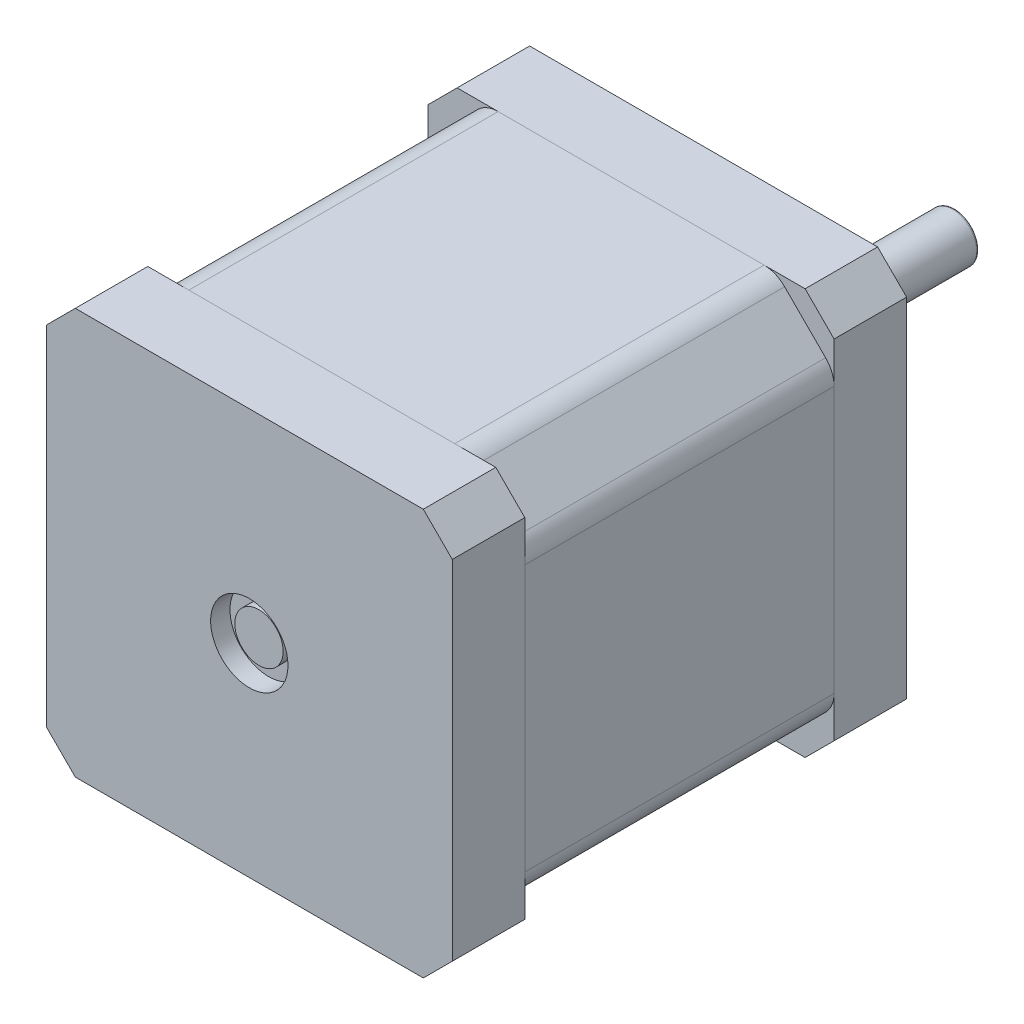
from build123d import *
from build123d.topology import SkipClean

# Parameters (mm, degrees)
IZIM1_R                     = 1.5
Y_KSEKLIK_EKSTR_ZYON1_DEPTH = 32
Y_KSEKLIK_EKSTR_ZYON2_START = 7.5
IZIM2_R                     = 1.5
Y_KSEKLIK_EKSTR_ZYON2_DEPTH = 7.5
IZIM3_R                     = 11
Y_KSEKLIK_EKSTR_ZYON3_DEPTH = 2
RADYUS1_R                   = 1
IZIM4_R                     = 4
KES_EKSTR_ZYON2_DEPTH       = 2
IZIM5_R                     = 2.5
Y_KSEKLIK_EKSTR_ZYON4_DEPTH = 26
IZIM6_W                     = 1.233072443
IZIM6_H                     = 4.616083878
KES_EKSTR_ZYON3_DEPTH       = 17
RADYUS2_R                   = 0.25
Y_KSEKLIK_EKSTR_ZYON5_DEPTH = 7.5
KES_EKSTR_ZYON4_START       = -2
IZIM8_R                     = 4
KES_EKSTR_ZYON4_DEPTH       = 2
Y_KSEKLIK_EKSTR_ZYON7_START = 1
IZIM10_R                    = 2.5
Y_KSEKLIK_EKSTR_ZYON7_DEPTH = 1
IZIM12_W                    = 1.322916666
IZIM12_H                    = 0.118723291
IZIM12_W_2                  = 1.356837607
Y_KSEKLIK_EKSTR_ZYON8_DEPTH = 0.1


with BuildPart() as part:
    # Çizim1 → Yükseklik-Ekstrüzyon1 (new body)
    with BuildSketch(Plane.XY):
        with BuildLine():
            Line((-15.878338215, 20.120978902), (-20.120978902, 15.878338215))
            ThreePointArc((-20.120978902, 15.878338215), (-20.771297156, 14.905068169), (-20.999658559, 13.757017872))
            Line((-20.999658559, 13.757017872), (-20.999658559, -13.757017872))
            ThreePointArc((-20.999658559, -13.757017872), (-20.771297156, -14.905068169), (-20.120978902, -15.878338215))
            Line((-20.120978902, -15.878338215), (-15.878338215, -20.120978902))
            ThreePointArc((-15.878338215, -20.120978902), (-14.905068169, -20.771297156), (-13.757017872, -20.999658559))
            Line((-13.757017872, -20.999658559), (13.757017872, -20.999658559))
            ThreePointArc((13.757017872, -20.999658559), (14.905068169, -20.771297156), (15.878338215, -20.120978902))
            Line((15.878338215, -20.120978902), (20.120978902, -15.878338215))
            ThreePointArc((20.120978902, -15.878338215), (20.771297156, -14.905068169), (20.999658559, -13.757017872))
            Line((20.999658559, -13.757017872), (20.999658559, 13.757017872))
            ThreePointArc((20.999658559, 13.757017872), (20.771297156, 14.905068169), (20.120978902, 15.878338215))
            Line((20.120978902, 15.878338215), (15.878338215, 20.120978902))
            ThreePointArc((15.878338215, 20.120978902), (14.905068169, 20.771297156), (13.757017872, 20.999658559))
            Line((13.757017872, 20.999658559), (-13.757017872, 20.999658559))
            ThreePointArc((-13.757017872, 20.999658559), (-14.905068169, 20.771297156), (-15.878338215, 20.120978902))
        make_face()
        with Locations((-15.5, 15.5)):
            Circle(IZIM1_R, mode=Mode.SUBTRACT)
        with Locations((15.5, 15.5)):
            Circle(IZIM1_R, mode=Mode.SUBTRACT)
        with Locations((15.5, -15.5)):
            Circle(IZIM1_R, mode=Mode.SUBTRACT)
        with Locations((-15.5, -15.5)):
            Circle(IZIM1_R, mode=Mode.SUBTRACT)
    extrude(amount=Y_KSEKLIK_EKSTR_ZYON1_DEPTH)

    # Çizim2 → Yükseklik-Ekstrüzyon2 (add)
    with SkipClean():  # the faces are left unmerged after this step: merging them gives an invalid solid
        with BuildSketch(Plane(origin=(0, 0, 0), x_dir=(-1, 0, 0), z_dir=(0, 0, -1)).offset(Y_KSEKLIK_EKSTR_ZYON2_START)):
            Polygon((-21, 18), (-18, 21), (18, 21), (21, 18), (21, -18), (18, -21), (-18, -21), (-21, -18), align=None)
            with Locations((-15.5, 15.5)):
                Circle(IZIM2_R, mode=Mode.SUBTRACT)
            with Locations((15.5, 15.5)):
                Circle(IZIM2_R, mode=Mode.SUBTRACT)
            with Locations((15.5, -15.5)):
                Circle(IZIM2_R, mode=Mode.SUBTRACT)
            with Locations((-15.5, -15.5)):
                Circle(IZIM2_R, mode=Mode.SUBTRACT)
        extrude(amount=-Y_KSEKLIK_EKSTR_ZYON2_DEPTH)

    # Çizim3 → Yükseklik-Ekstrüzyon3 (add)
    with SkipClean():  # the faces are left unmerged after this step: merging them gives an invalid solid
        with BuildSketch(Plane(origin=(0, 0, -7.5), x_dir=(-1, 0, 0), z_dir=(0, 0, -1))):
            with Locations(Location((0, 0, 0), (0, 0, 180))):
                Circle(IZIM3_R)
        extrude(amount=Y_KSEKLIK_EKSTR_ZYON3_DEPTH)

    # Radyus1
    radyus1_edges = [part.edges().sort_by_distance(p)[0] for p in [
        (-11, 0, -7.5),
    ]]
    fillet(radyus1_edges, radius=RADYUS1_R)

    # Çizim4 → Kes-Ekstrüzyon2 (cut)
    with BuildSketch(Plane(origin=(0, 0, -9.5), x_dir=(-1, 0, 0), z_dir=(0, 0, -1))):
        Circle(IZIM4_R)
    extrude(amount=-KES_EKSTR_ZYON2_DEPTH, mode=Mode.SUBTRACT)

    # Çizim5 → Yükseklik-Ekstrüzyon4 (add)
    with BuildSketch(Plane(origin=(0, 0, -7.5), x_dir=(-1, 0, 0), z_dir=(0, 0, -1))):
        with Locations(Location((0, 0, 0), (0, 0, 180))):
            Circle(IZIM5_R)
    extrude(amount=Y_KSEKLIK_EKSTR_ZYON4_DEPTH)

    # Çizim6 → Kes-Ekstrüzyon3 (cut)
    with BuildSketch(Plane(origin=(0, 0, -33.5), x_dir=(-1, 0, 0), z_dir=(0, 0, -1))):
        with Locations((2.616536222, -0.191958061)):
            Rectangle(IZIM6_W, IZIM6_H)
    extrude(amount=-KES_EKSTR_ZYON3_DEPTH, mode=Mode.SUBTRACT)

    # Radyus2
    radyus2_edges = [part.edges().sort_by_distance(p)[0] for p in [
        (0.790569415, 2.371708245, -33.5),
        (-2, 0, -33.5),
    ]]
    fillet(radyus2_edges, radius=RADYUS2_R)

    # Çizim7 → Yükseklik-Ekstrüzyon5 (add)
    with BuildSketch(Plane.XY.offset(32)):
        Polygon((-18, 21), (18, 21), (21, 18), (21, -18), (18, -21), (-18, -21), (-21, -18), (-21, 18), align=None)
    extrude(amount=Y_KSEKLIK_EKSTR_ZYON5_DEPTH)

    # Çizim8 → Kes-Ekstrüzyon4 (cut)
    with BuildSketch(Plane.XY.offset(39.5).offset(KES_EKSTR_ZYON4_START)):
        with Locations(Location((0, 0, 0), (0, 0, 180))):
            Circle(IZIM8_R)
    extrude(amount=KES_EKSTR_ZYON4_DEPTH, mode=Mode.SUBTRACT)

    # Çizim10 → Yükseklik-Ekstrüzyon7 (add)
    with BuildSketch(Plane.XY.offset(37.5).offset(Y_KSEKLIK_EKSTR_ZYON7_START)):
        with Locations(Location((0, 0, 0), (0, 0, 216.869897646))):
            Circle(IZIM10_R)
    extrude(amount=-Y_KSEKLIK_EKSTR_ZYON7_DEPTH)

    # Çizim12 → Yükseklik-Ekstrüzyon8 (add)
    # profile 1 of 54: a face of its own
    with BuildSketch(Plane.ZY.offset(20.999658559)):
        with BuildLine():
            Line((7.410133378, -7.700053419), (7.34308652, -7.588220319))
            add(Edge.make_bspline(
                [(7.34308652, -7.588220319), (7.36049776, -7.577819081), (7.393857026, -7.557890709), (7.438933725, -7.524647189), (7.477246207, -7.490201119), (7.508571592, -7.454297412), (7.533234117, -7.417155224), (7.550697461, -7.378532084), (7.561589214, -7.33855815), (7.562912163, -7.311353759), (7.563572631, -7.297772269)],
                knots=[0, 0, 0, 0, 1.272034388, 2.437168799, 3.508375237, 4.49857839, 5.41946034, 6.295179144, 7.148887113, 8, 8, 8, 8], degree=3))
            add(Edge.make_bspline(
                [(7.563572631, -7.297772269), (7.563241899, -7.286175715), (7.562586224, -7.263185518), (7.55654057, -7.22927391), (7.546649892, -7.196503749), (7.533242008, -7.165200789), (7.516760804, -7.136194355), (7.49732637, -7.110350647), (7.474870578, -7.088528376), (7.450225308, -7.070437449), (7.423797314, -7.056438822), (7.396567019, -7.045858523), (7.368160805, -7.039932986), (7.349030489, -7.039043807), (7.339376417, -7.038595085)],
                knots=[0, 0, 0, 0, 1.09553864, 2.171907928, 3.244545276, 4.325730702, 5.384330216, 6.391480148, 7.371786628, 8.333890167, 9.27165687, 10.191402356, 11.087295184, 12, 12, 12, 12], degree=3))
            add(Edge.make_bspline(
                [(7.339376417, -7.038595085), (7.328358193, -7.039140371), (7.306045089, -7.040244634), (7.273068398, -7.049976578), (7.240293228, -7.064836848), (7.220015855, -7.078803832), (7.209522818, -7.0860314)],
                knots=[0, 0, 0, 0, 0.938992559, 1.901562324, 2.914110574, 4, 4, 4, 4], degree=3))
            add(Edge.make_bspline(
                [(7.209522818, -7.0860314), (7.201944638, -7.091953651), (7.186035197, -7.104386676), (7.16237361, -7.125779315), (7.137917249, -7.150754321), (7.112129208, -7.178969871), (7.085223682, -7.210473294), (7.056990712, -7.245276778), (7.028007242, -7.283677353), (7.008593923, -7.310630586), (6.998576971, -7.324538011)],
                knots=[0, 0, 0, 0, 0.72225051, 1.516274602, 2.393638633, 3.3469932, 4.386926276, 5.505032946, 6.712638081, 8, 8, 8, 8], degree=3))
            add(Edge.make_bspline(
                [(6.998576971, -7.324538011), (6.988663189, -7.338456605), (6.969708794, -7.365067896), (6.941578186, -7.402282896), (6.915859224, -7.435561607), (6.892309791, -7.464756116), (6.870926693, -7.489853583), (6.85191527, -7.511051777), (6.834761364, -7.527810695), (6.823633238, -7.537129918), (6.818636984, -7.541314019)],
                knots=[0, 0, 0, 0, 1.452282411, 2.77665338, 3.964542531, 5.026858415, 5.96415736, 6.766646006, 7.446254459, 8, 8, 8, 8], degree=3))
            add(Edge.make_bspline(
                [(6.818636984, -7.541314019), (6.810849896, -7.547161293), (6.795535542, -7.558660741), (6.771605762, -7.573856503), (6.747156339, -7.58667113), (6.722098665, -7.596984509), (6.696621062, -7.605324548), (6.670532254, -7.611123015), (6.644009348, -7.614697067), (6.626164386, -7.615066256), (6.617231401, -7.615251068)],
                knots=[0, 0, 0, 0, 1.068019517, 2.100403715, 3.106014851, 4.09224787, 5.069873182, 6.043214339, 7.020455327, 8, 8, 8, 8], degree=3))
            add(Edge.make_bspline(
                [(6.617231401, -7.615251068), (6.603235001, -7.614757752), (6.575541363, -7.613781665), (6.535086655, -7.605526151), (6.496461142, -7.592497405), (6.460056127, -7.574238627), (6.426786295, -7.550723512), (6.396352185, -7.523392346), (6.370417895, -7.491140826), (6.348111682, -7.455435996), (6.330471825, -7.416559596), (6.31768816, -7.3756312), (6.310094823, -7.332945015), (6.309035401, -7.303986), (6.308497844, -7.289292034)],
                knots=[0, 0, 0, 0, 1.005248779, 1.989011071, 2.95484373, 3.928844559, 4.904706341, 5.875556129, 6.859318422, 7.868909462, 8.894684146, 9.918924798, 10.944050749, 12, 12, 12, 12], degree=3))
            add(Edge.make_bspline(
                [(6.308497844, -7.289292034), (6.309028234, -7.273700222), (6.31008301, -7.242693084), (6.31948225, -7.19715613), (6.334441566, -7.153134146), (6.351992763, -7.117878326), (6.369410637, -7.090226948), (6.385310058, -7.069160409), (6.403576245, -7.047696583), (6.424594278, -7.026066143), (6.447943776, -7.004055551), (6.473822392, -6.981766193), (6.50199692, -6.95898948), (6.522115374, -6.944341511), (6.532429051, -6.936832265)],
                knots=[0, 0, 0, 0, 1.286507425, 2.558452658, 3.822738219, 5.118007103, 5.800084425, 6.519418873, 7.295692132, 8.12638276, 9.008892966, 9.945018126, 10.946518512, 12, 12, 12, 12], degree=3))
            Line((6.532429051, -6.936832265), (6.613786306, -7.04416024))
            add(Edge.make_bspline(
                [(6.613786306, -7.04416024), (6.605436824, -7.050640521), (6.589357673, -7.063120029), (6.566847561, -7.082074067), (6.546257648, -7.099911633), (6.52842074, -7.117620434), (6.512001139, -7.133835482), (6.498192787, -7.149852668), (6.486559406, -7.165053886), (6.474121772, -7.184168997), (6.462165698, -7.208383464), (6.451663692, -7.238526579), (6.445433341, -7.270133828), (6.444602308, -7.291650018), (6.444181605, -7.302542401)],
                knots=[0, 0, 0, 0, 1.181392137, 2.275085037, 3.289537922, 4.225335853, 5.084247276, 5.86831218, 6.587234301, 7.222706459, 8.415108401, 9.595592188, 10.782789524, 12, 12, 12, 12], degree=3))
            add(Edge.make_bspline(
                [(6.444181605, -7.302542401), (6.444632099, -7.316211931), (6.445500835, -7.342572331), (6.455238399, -7.379909194), (6.470043709, -7.413708372), (6.491392811, -7.442679587), (6.516845053, -7.466600671), (6.545871543, -7.484118996), (6.577930171, -7.494592895), (6.600282543, -7.495874882), (6.611666247, -7.496527778)],
                knots=[0, 0, 0, 0, 1.144248881, 2.206576175, 3.214949548, 4.222996039, 5.203671638, 6.127710127, 7.046472867, 8, 8, 8, 8], degree=3))
            add(Edge.make_bspline(
                [(6.611666247, -7.496527778), (6.618752234, -7.496370697), (6.633022919, -7.496054346), (6.654006309, -7.492011897), (6.674879059, -7.486546175), (6.69556771, -7.47816696), (6.716540742, -7.466498209), (6.738094381, -7.451191307), (6.760414279, -7.431908532), (6.774931388, -7.417138496), (6.782595985, -7.409340361)],
                knots=[0, 0, 0, 0, 0.858259122, 1.72847414, 2.583651051, 3.473048463, 4.427392529, 5.488649985, 6.674082839, 8, 8, 8, 8], degree=3))
            add(Edge.make_bspline(
                [(6.782595985, -7.409340361), (6.785180218, -7.406444545), (6.791319764, -7.399564748), (6.801371013, -7.38698724), (6.81376968, -7.370377909), (6.829110719, -7.35017047), (6.846906391, -7.32599233), (6.866929155, -7.297840831), (6.889829016, -7.266029776), (6.905839157, -7.243456313), (6.914304635, -7.231520433)],
                knots=[0, 0, 0, 0, 0.420754252, 0.999615792, 1.744751191, 2.668019286, 3.750313428, 4.999500688, 6.413464383, 8, 8, 8, 8], degree=3))
            add(Edge.make_bspline(
                [(6.914304635, -7.231520433), (6.924752418, -7.217162672), (6.944983102, -7.189360858), (6.975378215, -7.149802648), (7.005105541, -7.113935517), (7.03397331, -7.081630885), (7.061769002, -7.052578493), (7.088805477, -7.027071206), (7.114905432, -7.004993291), (7.148139652, -6.980900237), (7.189334684, -6.956573395), (7.239829118, -6.935715127), (7.290468456, -6.922445454), (7.324460196, -6.92072209), (7.341231468, -6.919871795)],
                knots=[0, 0, 0, 0, 1.163604038, 2.253157948, 3.268574773, 4.215621239, 5.091738613, 5.902582348, 6.650434646, 7.330118262, 8.591011492, 9.77460283, 10.902005569, 12, 12, 12, 12], degree=3))
            add(Edge.make_bspline(
                [(7.341231468, -6.919871795), (7.353091617, -6.920120431), (7.3765816, -6.920612874), (7.411075673, -6.926264062), (7.444569237, -6.934562864), (7.476615159, -6.946970264), (7.507727624, -6.962360899), (7.537320534, -6.981610151), (7.565968816, -7.004039174), (7.592869309, -7.029754736), (7.617594329, -7.057879064), (7.639497485, -7.087711534), (7.658181052, -7.118940723), (7.673060681, -7.151904821), (7.684776614, -7.186249706), (7.693241625, -7.222088636), (7.698442725, -7.259457914), (7.698982141, -7.28485824), (7.699256391, -7.297772269)],
                knots=[0, 0, 0, 0, 0.983922938, 1.948738757, 2.895227473, 3.844781104, 4.796118043, 5.772795661, 6.770647148, 7.813532943, 8.8582745, 9.876489951, 10.882905461, 11.874265028, 12.874055871, 13.891769171, 14.928133632, 16, 16, 16, 16], degree=3))
            add(Edge.make_bspline(
                [(7.699256391, -7.297772269), (7.699063177, -7.307764199), (7.698679181, -7.327622222), (7.695284471, -7.356994556), (7.690481488, -7.385773506), (7.682856174, -7.413597958), (7.673604442, -7.440826364), (7.662212935, -7.467340424), (7.648561248, -7.49315253), (7.632953651, -7.518409086), (7.614785313, -7.543039089), (7.593643233, -7.566838227), (7.570066528, -7.590432592), (7.543690977, -7.613654811), (7.514226541, -7.635998249), (7.482112104, -7.657999302), (7.447252166, -7.679550746), (7.422737408, -7.693091546), (7.410133378, -7.700053419)],
                knots=[0, 0, 0, 0, 0.915313873, 1.819100311, 2.706792138, 3.586475221, 4.459428225, 5.3405999, 6.2277379, 7.133009489, 8.059106158, 9.028520402, 10.047404263, 11.114294124, 12.246039232, 13.433834781, 14.680630578, 16, 16, 16, 16], degree=3))
        make_face()
    # profile 2 of 54: a face of its own
    with BuildSketch(Plane.ZY.offset(20.999658559)):
        Polygon((6.478102545, -6.801148504), (6.342418785, -6.801148504), (6.342418785, -6.105769231), (6.478102545, -6.105769231), (6.478102545, -6.394097222), (7.665335451, -6.394097222), (7.665335451, -6.512820513), (6.478102545, -6.512820513), align=None)
    # profile 3 of 54: a face of its own
    with BuildSketch(Plane.ZY.offset(20.999658559)):
        Polygon((6.342418785, -5.86832265), (6.342418785, -5.122061966), (6.478102545, -5.122061966), (6.478102545, -5.749599359), (6.885153827, -5.749599359), (6.885153827, -5.122061966), (7.020837588, -5.122061966), (7.020837588, -5.749599359), (7.529651691, -5.749599359), (7.529651691, -5.122061966), (7.665335451, -5.122061966), (7.665335451, -5.86832265), align=None)
    # profile 4 of 54: a face of its own
    with BuildSketch(Plane.ZY.offset(20.999658559)):
        with BuildLine():
            Line((6.342418785, -4.884615385), (6.342418785, -4.625173194))
            add(Edge.make_bspline(
                [(6.342418785, -4.625173194), (6.3424384, -4.607328595), (6.342475984, -4.573137552), (6.343615486, -4.52410835), (6.34513748, -4.479579076), (6.347247303, -4.439645748), (6.349740657, -4.404185496), (6.353237708, -4.373358779), (6.356889069, -4.346923292), (6.360601327, -4.331083652), (6.362294335, -4.323859842)],
                knots=[0, 0, 0, 0, 1.415646017, 2.712440637, 3.8905458, 4.950247383, 5.884950622, 6.709939814, 7.411656543, 8, 8, 8, 8], degree=3))
            add(Edge.make_bspline(
                [(6.362294335, -4.323859842), (6.364797373, -4.314715342), (6.369744466, -4.296641821), (6.379651213, -4.270597713), (6.391404792, -4.245824205), (6.40477475, -4.222210724), (6.42041922, -4.200187354), (6.437297441, -4.179019933), (6.456500154, -4.159455669), (6.477421702, -4.141229568), (6.499796733, -4.124383688), (6.524031773, -4.110230103), (6.549403275, -4.097854649), (6.576256059, -4.087722237), (6.604616194, -4.080187354), (6.634282136, -4.074593463), (6.665287244, -4.071026591), (6.686476824, -4.070686134), (6.69726362, -4.070512821)],
                knots=[0, 0, 0, 0, 0.999549623, 1.97554611, 2.93413192, 3.889860808, 4.833293765, 5.780583482, 6.742559327, 7.719844669, 8.705620613, 9.691528643, 10.674968152, 11.680406189, 12.713313868, 13.765869198, 14.862690416, 16, 16, 16, 16], degree=3))
            add(Edge.make_bspline(
                [(6.69726362, -4.070512821), (6.708140934, -4.070672109), (6.729423134, -4.070983768), (6.760558087, -4.074724328), (6.790311764, -4.079762823), (6.818618194, -4.087510221), (6.845309273, -4.097657246), (6.870792894, -4.109560492), (6.894635508, -4.123917362), (6.916923674, -4.140414069), (6.937678314, -4.158765415), (6.956749025, -4.178893758), (6.974024177, -4.200717836), (6.989542497, -4.224168291), (7.002944126, -4.24947374), (7.014947632, -4.276250387), (7.025028657, -4.304730975), (7.030331687, -4.324439603), (7.033027926, -4.334460136)],
                knots=[0, 0, 0, 0, 1.121902311, 2.195077645, 3.232258892, 4.234102512, 5.217864754, 6.176164875, 7.132989551, 8.084763148, 9.034132444, 9.988522005, 10.94243251, 11.903244335, 12.886203696, 13.894208494, 14.929344452, 16, 16, 16, 16], degree=3))
            add(Edge.make_bspline(
                [(7.033027926, -4.334460136), (7.034789108, -4.342748241), (7.038648842, -4.360912104), (7.042987074, -4.390824293), (7.046544898, -4.425668641), (7.049865088, -4.465326593), (7.051624374, -4.509890629), (7.053690063, -4.559258542), (7.054664748, -4.613597409), (7.05472636, -4.651497075), (7.054758528, -4.671284472)],
                knots=[0, 0, 0, 0, 0.601372724, 1.317943291, 2.144091499, 3.08771165, 4.142394186, 5.309582461, 6.595334295, 8, 8, 8, 8], degree=3))
            Line((7.054758528, -4.671284472), (7.054758528, -4.765892094))
            Line((7.054758528, -4.765892094), (7.665335451, -4.765892094))
            Line((7.665335451, -4.765892094), (7.665335451, -4.884615385))
            Line((7.665335451, -4.884615385), (6.342418785, -4.884615385))
        make_face()
        with BuildLine():
            Line((6.478102545, -4.765892094), (6.919074767, -4.765892094))
            Line((6.919074767, -4.765892094), (6.921989848, -4.534275674))
            add(Edge.make_bspline(
                [(6.921989848, -4.534275674), (6.921996076, -4.522966576), (6.922008097, -4.501134594), (6.920496662, -4.469598746), (6.918775131, -4.440336289), (6.916171416, -4.413457262), (6.912758357, -4.388867353), (6.908513877, -4.366778957), (6.903899452, -4.346861707), (6.896189893, -4.323950769), (6.884335655, -4.29819812), (6.867079167, -4.270065317), (6.844724212, -4.246407722), (6.819659579, -4.225973134), (6.791851302, -4.209437792), (6.761941601, -4.197772768), (6.730373585, -4.190589928), (6.708785412, -4.18969286), (6.697793634, -4.189236111)],
                knots=[0, 0, 0, 0, 1.160746174, 2.240796558, 3.240300023, 4.169675897, 5.012224395, 5.787635701, 6.478238024, 7.109103438, 8.265591281, 9.382545711, 10.479929969, 11.588830844, 12.694575677, 13.785760505, 14.872603606, 16, 16, 16, 16], degree=3))
            add(Edge.make_bspline(
                [(6.697793634, -4.189236111), (6.687157957, -4.189713366), (6.666015546, -4.19066209), (6.635029373, -4.197713492), (6.605458724, -4.209563053), (6.577874391, -4.22598759), (6.552864911, -4.245926262), (6.531102271, -4.269082266), (6.513724279, -4.295514843), (6.502075761, -4.31989827), (6.495255964, -4.341733328), (6.490330274, -4.360605607), (6.486933671, -4.382023437), (6.483683545, -4.405783316), (6.481060045, -4.431855077), (6.479238187, -4.460404425), (6.478183137, -4.49133629), (6.47813006, -4.512809232), (6.478102545, -4.523940388)],
                knots=[0, 0, 0, 0, 1.120540835, 2.227496496, 3.330685923, 4.466139262, 5.598993257, 6.692710361, 7.80064471, 8.921224235, 9.527843361, 10.209888745, 10.975318552, 11.811557897, 12.738105936, 13.73658638, 14.826690375, 16, 16, 16, 16], degree=3))
            Line((6.478102545, -4.523940388), (6.478102545, -4.765892094))
        make_face(mode=Mode.SUBTRACT)
    # profile 5 of 54: a face of its own
    with BuildSketch(Plane.ZY.offset(20.999658559)):
        with BuildLine():
            Line((6.342418785, -3.799145299), (6.342418785, -3.539703108))
            add(Edge.make_bspline(
                [(6.342418785, -3.539703108), (6.3424384, -3.52185851), (6.342475984, -3.487667467), (6.343615486, -3.438638264), (6.34513748, -3.394108991), (6.347247303, -3.354175662), (6.349740657, -3.318715411), (6.353237708, -3.287888693), (6.356889069, -3.261453206), (6.360601327, -3.245613566), (6.362294335, -3.238389757)],
                knots=[0, 0, 0, 0, 1.415646017, 2.712440637, 3.8905458, 4.950247383, 5.884950622, 6.709939814, 7.411656543, 8, 8, 8, 8], degree=3))
            add(Edge.make_bspline(
                [(6.362294335, -3.238389757), (6.364797373, -3.229245257), (6.369744466, -3.211171736), (6.379651213, -3.185127628), (6.391404792, -3.160354119), (6.40477475, -3.136740639), (6.42041922, -3.114717269), (6.437297441, -3.093549847), (6.456500154, -3.073985584), (6.477421702, -3.055759482), (6.499796733, -3.038913603), (6.524031773, -3.024760017), (6.549403275, -3.012384564), (6.576256059, -3.002252151), (6.604616194, -2.994717269), (6.634282136, -2.989123377), (6.665287244, -2.985556506), (6.686476824, -2.985216049), (6.69726362, -2.985042735)],
                knots=[0, 0, 0, 0, 0.999549623, 1.97554611, 2.93413192, 3.889860808, 4.833293765, 5.780583482, 6.742559327, 7.719844669, 8.705620613, 9.691528643, 10.674968152, 11.680406189, 12.713313868, 13.765869198, 14.862690416, 16, 16, 16, 16], degree=3))
            add(Edge.make_bspline(
                [(6.69726362, -2.985042735), (6.708140934, -2.985202024), (6.729423134, -2.985513682), (6.760558087, -2.989254243), (6.790311764, -2.994292738), (6.818618194, -3.002040135), (6.845309273, -3.012187161), (6.870792894, -3.024090407), (6.894635508, -3.038447277), (6.916923674, -3.054943983), (6.937678314, -3.07329533), (6.956749025, -3.093423673), (6.974024177, -3.115247751), (6.989542497, -3.138698205), (7.002944126, -3.164003654), (7.014947632, -3.190780301), (7.025028657, -3.219260889), (7.030331687, -3.238969518), (7.033027926, -3.248990051)],
                knots=[0, 0, 0, 0, 1.121902311, 2.195077645, 3.232258892, 4.234102512, 5.217864754, 6.176164875, 7.132989551, 8.084763148, 9.034132444, 9.988522005, 10.94243251, 11.903244335, 12.886203696, 13.894208494, 14.929344452, 16, 16, 16, 16], degree=3))
            add(Edge.make_bspline(
                [(7.033027926, -3.248990051), (7.034789108, -3.257278155), (7.038648842, -3.275442018), (7.042987074, -3.305354207), (7.046544898, -3.340198556), (7.049865088, -3.379856507), (7.051624374, -3.424420544), (7.053690063, -3.473788457), (7.054664748, -3.528127324), (7.05472636, -3.566026989), (7.054758528, -3.585814386)],
                knots=[0, 0, 0, 0, 0.601372724, 1.317943291, 2.144091499, 3.08771165, 4.142394186, 5.309582461, 6.595334295, 8, 8, 8, 8], degree=3))
            Line((7.054758528, -3.585814386), (7.054758528, -3.680422009))
            Line((7.054758528, -3.680422009), (7.665335451, -3.680422009))
            Line((7.665335451, -3.680422009), (7.665335451, -3.799145299))
            Line((7.665335451, -3.799145299), (6.342418785, -3.799145299))
        make_face()
        with BuildLine():
            Line((6.478102545, -3.680422009), (6.919074767, -3.680422009))
            Line((6.919074767, -3.680422009), (6.921989848, -3.448805589))
            add(Edge.make_bspline(
                [(6.921989848, -3.448805589), (6.921996076, -3.43749649), (6.922008097, -3.415664508), (6.920496662, -3.38412866), (6.918775131, -3.354866203), (6.916171416, -3.327987177), (6.912758357, -3.303397267), (6.908513877, -3.281308871), (6.903899452, -3.261391621), (6.896189893, -3.238480683), (6.884335655, -3.212728034), (6.867079167, -3.184595231), (6.844724212, -3.160937636), (6.819659579, -3.140503048), (6.791851302, -3.123967707), (6.761941601, -3.112302683), (6.730373585, -3.105119842), (6.708785412, -3.104222774), (6.697793634, -3.103766026)],
                knots=[0, 0, 0, 0, 1.160746174, 2.240796558, 3.240300023, 4.169675897, 5.012224395, 5.787635701, 6.478238024, 7.109103438, 8.265591281, 9.382545711, 10.479929969, 11.588830844, 12.694575677, 13.785760505, 14.872603606, 16, 16, 16, 16], degree=3))
            add(Edge.make_bspline(
                [(6.697793634, -3.103766026), (6.687157957, -3.104243281), (6.666015546, -3.105192005), (6.635029373, -3.112243407), (6.605458724, -3.124092967), (6.577874391, -3.140517504), (6.552864911, -3.160456176), (6.531102271, -3.183612181), (6.513724279, -3.210044757), (6.502075761, -3.234428184), (6.495255964, -3.256263243), (6.490330274, -3.275135522), (6.486933671, -3.296553352), (6.483683545, -3.320313231), (6.481060045, -3.346384991), (6.479238187, -3.37493434), (6.478183137, -3.405866204), (6.47813006, -3.427339147), (6.478102545, -3.438470302)],
                knots=[0, 0, 0, 0, 1.120540835, 2.227496496, 3.330685923, 4.466139262, 5.598993257, 6.692710361, 7.80064471, 8.921224235, 9.527843361, 10.209888745, 10.975318552, 11.811557897, 12.738105936, 13.73658638, 14.826690375, 16, 16, 16, 16], degree=3))
            Line((6.478102545, -3.438470302), (6.478102545, -3.680422009))
        make_face(mode=Mode.SUBTRACT)
    # profile 6 of 54: a face of its own
    with BuildSketch(Plane.ZY.offset(20.999658559)):
        with Locations((7.003877118, -2.654313569)):
            Rectangle(IZIM12_W, IZIM12_H)
    # profile 7 of 54: a face of its own
    with BuildSketch(Plane.ZY.offset(20.999658559)):
        Polygon((7.665335451, -2.306623932), (6.342418785, -2.306623932), (6.342418785, -2.281713241), (7.383632643, -1.407719017), (6.342418785, -1.407719017), (6.342418785, -1.288995726), (7.665335451, -1.288995726), (7.665335451, -1.316026476), (6.626506658, -2.187900641), (7.665335451, -2.187900641), align=None)
    # profile 8 of 54: a face of its own
    with BuildSketch(Plane.ZY.offset(20.999658559)):
        with BuildLine():
            Line((6.568205043, 0.288327991), (6.664667716, 0.186565171))
            add(Edge.make_bspline(
                [(6.664667716, 0.186565171), (6.647338936, 0.168154298), (6.61309459, 0.131771571), (6.568734268, 0.072353735), (6.530357239, 0.010609112), (6.499364858, -0.053562135), (6.475052802, -0.118477278), (6.457380161, -0.183020097), (6.446188225, -0.246772698), (6.444843984, -0.289168134), (6.444181605, -0.310058594)],
                knots=[0, 0, 0, 0, 1.089067066, 2.152164705, 3.18986567, 4.218445106, 5.218487318, 6.173592265, 7.100032889, 8, 8, 8, 8], degree=3))
            add(Edge.make_bspline(
                [(6.444181605, -0.310058594), (6.444337938, -0.322877543), (6.444650199, -0.348482194), (6.448635661, -0.386514894), (6.454367619, -0.424148712), (6.462661126, -0.461312606), (6.473172288, -0.498078837), (6.486320367, -0.53431953), (6.501649279, -0.570102298), (6.519362195, -0.605090049), (6.538820287, -0.63900991), (6.560383512, -0.671045658), (6.583359371, -0.701403369), (6.608328204, -0.729505599), (6.635045188, -0.755539281), (6.663029172, -0.779983266), (6.692830354, -0.802381976), (6.724326184, -0.822333691), (6.756783927, -0.840350906), (6.789928308, -0.855920577), (6.823451641, -0.869455887), (6.85760635, -0.879764795), (6.892040314, -0.888496376), (6.926933984, -0.8945747), (6.962378481, -0.898012891), (6.986114516, -0.898606499), (6.998046956, -0.898904915)],
                knots=[0, 0, 0, 0, 1.028150113, 2.053633673, 3.06513288, 4.081487945, 5.106702018, 6.131327874, 7.172780699, 8.228344599, 9.276313556, 10.308389736, 11.324843658, 12.329040066, 13.321460474, 14.316307835, 15.308626991, 16.309440696, 17.305625405, 18.28535951, 19.246194545, 20.203493668, 21.145557131, 22.095268976, 23.042464743, 24, 24, 24, 24], degree=3))
            add(Edge.make_bspline(
                [(6.998046956, -0.898904915), (7.010244498, -0.898619091), (7.034606274, -0.898048224), (7.070966223, -0.894399545), (7.106781955, -0.887612903), (7.142109803, -0.878612629), (7.177020076, -0.867170278), (7.211476341, -0.853112393), (7.24547525, -0.83636573), (7.278679293, -0.817024209), (7.310996307, -0.795664975), (7.341692691, -0.772173308), (7.370411215, -0.746509656), (7.397571353, -0.719144579), (7.423001696, -0.689828747), (7.44639572, -0.65827774), (7.46811517, -0.624933212), (7.487921438, -0.589780372), (7.505613508, -0.553190773), (7.521346469, -0.515674205), (7.53430321, -0.477110087), (7.544863157, -0.437701282), (7.553518922, -0.397494715), (7.559087449, -0.356286314), (7.563128328, -0.31437907), (7.563423781, -0.286129647), (7.563572631, -0.271897536)],
                knots=[0, 0, 0, 0, 0.935915162, 1.869274651, 2.799799983, 3.730201895, 4.664668062, 5.616159355, 6.583070886, 7.570012957, 8.562524459, 9.553461134, 10.53281078, 11.515274572, 12.509912756, 13.507571325, 14.526460018, 15.561318395, 16.601025881, 17.643204557, 18.680545676, 19.719612342, 20.772381578, 21.833430283, 22.908478249, 24, 24, 24, 24], degree=3))
            add(Edge.make_bspline(
                [(7.563572631, -0.271897536), (7.56321424, -0.254745531), (7.562510482, -0.221064784), (7.557027608, -0.171556018), (7.548475341, -0.124001844), (7.535911771, -0.078557072), (7.520009387, -0.035056777), (7.500343823, 0.006338604), (7.477121992, 0.045743375), (7.450814133, 0.08298698), (7.421502659, 0.117184006), (7.390155315, 0.148307351), (7.35636597, 0.17528677), (7.320638205, 0.198928167), (7.282630278, 0.218468494), (7.242553627, 0.234512026), (7.200383457, 0.24680852), (7.171244698, 0.251856425), (7.156521349, 0.254407051)],
                knots=[0, 0, 0, 0, 1.130199668, 2.219330667, 3.279027493, 4.311506524, 5.322739849, 6.327972234, 7.327472899, 8.33386792, 9.329086447, 10.29244429, 11.240784345, 12.174119183, 13.111530729, 14.052100829, 15.015757696, 16, 16, 16, 16], degree=3))
            Line((7.156521349, 0.254407051), (7.156521349, -0.186565171))
            Line((7.156521349, -0.186565171), (7.020837588, -0.186565171))
            Line((7.020837588, -0.186565171), (7.020837588, 0.373130342))
            add(Edge.make_bspline(
                [(7.020837588, 0.373130342), (7.046127026, 0.372485572), (7.095623024, 0.37122364), (7.167805239, 0.362371848), (7.235981445, 0.348078107), (7.300223439, 0.328551739), (7.360440184, 0.303274475), (7.416692818, 0.272517597), (7.468617932, 0.235788849), (7.516639431, 0.194396509), (7.559475175, 0.147943251), (7.597123848, 0.097684279), (7.628837038, 0.043536556), (7.654637944, -0.014448699), (7.674774245, -0.07608166), (7.689051002, -0.141504947), (7.697604589, -0.210629838), (7.698697462, -0.258004117), (7.699256391, -0.282232823)],
                knots=[0, 0, 0, 0, 1.140356446, 2.231883559, 3.274166699, 4.278491846, 5.25512956, 6.21435461, 7.1637429, 8.11826594, 9.068280886, 10.0076534, 10.945064095, 11.891975133, 12.864533718, 13.863980011, 14.907571808, 16, 16, 16, 16], degree=3))
            add(Edge.make_bspline(
                [(7.699256391, -0.282232823), (7.699041277, -0.297166713), (7.698617002, -0.326621158), (7.695601755, -0.370122789), (7.69095999, -0.412424984), (7.683950374, -0.453521583), (7.675364776, -0.493563754), (7.664370689, -0.532351514), (7.651644722, -0.570032619), (7.637169869, -0.60666531), (7.62039844, -0.641917088), (7.60176057, -0.675944968), (7.581352365, -0.708937045), (7.558820885, -0.740668587), (7.534334657, -0.771304926), (7.507844605, -0.800648519), (7.479431711, -0.828863639), (7.459255716, -0.846537981), (7.449089458, -0.85544371)],
                knots=[0, 0, 0, 0, 1.107784379, 2.184907829, 3.233506516, 4.263428166, 5.276301166, 6.270063455, 7.25232949, 8.225834625, 9.190232166, 10.146266622, 11.1027726, 12.066435141, 13.031522626, 14.010570082, 14.99756817, 16, 16, 16, 16], degree=3))
            add(Edge.make_bspline(
                [(7.449089458, -0.85544371), (7.432960967, -0.868365178), (7.400971701, -0.893993632), (7.349718151, -0.926982697), (7.296649591, -0.955104656), (7.241618288, -0.977922255), (7.184675716, -0.99573933), (7.125894639, -1.008517288), (7.065199362, -1.016003972), (7.024126479, -1.017082541), (7.003347103, -1.017628205)],
                knots=[0, 0, 0, 0, 1.023165419, 2.029347347, 3.013907458, 3.994755782, 4.975994455, 5.96558838, 6.970761222, 8, 8, 8, 8], degree=3))
            add(Edge.make_bspline(
                [(7.003347103, -1.017628205), (6.98778724, -1.017427032), (6.956865269, -1.017027242), (6.9109573, -1.012179502), (6.865864476, -1.005224206), (6.821623673, -0.995001055), (6.778205295, -0.982113509), (6.735589357, -0.966029193), (6.693750056, -0.947302825), (6.652977845, -0.925535283), (6.613804539, -0.901318825), (6.576421836, -0.875008789), (6.541435597, -0.846402158), (6.508764775, -0.815415634), (6.477925148, -0.782673851), (6.449560908, -0.747489445), (6.4232282, -0.710395491), (6.399433008, -0.671104435), (6.378051706, -0.630236277), (6.359308592, -0.587879855), (6.343817759, -0.54405056), (6.33067413, -0.499076097), (6.320954411, -0.452616216), (6.313905631, -0.40500802), (6.309082428, -0.356003365), (6.308694527, -0.322879033), (6.308497844, -0.306083484)],
                knots=[0, 0, 0, 0, 1.00895651, 2.005089799, 2.991467152, 3.967318338, 4.948153826, 5.927364234, 6.919980553, 7.91976625, 8.923240147, 9.905815003, 10.88314567, 11.851989312, 12.825009789, 13.798721852, 14.781296708, 15.773896486, 16.776076962, 17.771600213, 18.775744723, 19.78957137, 20.808953803, 21.851964491, 22.910847925, 24, 24, 24, 24], degree=3))
            add(Edge.make_bspline(
                [(6.308497844, -0.306083484), (6.308716878, -0.29238629), (6.309151197, -0.265226366), (6.312161645, -0.224810985), (6.316933171, -0.185020292), (6.323444486, -0.145795287), (6.332313203, -0.107269547), (6.342926126, -0.069333322), (6.355282856, -0.03193162), (6.370019712, 0.004818343), (6.386746528, 0.041163671), (6.405574816, 0.07730645), (6.426826529, 0.113123188), (6.45056477, 0.148676), (6.476381836, 0.184189077), (6.505016112, 0.219100713), (6.535338403, 0.254253611), (6.557140895, 0.276857273), (6.568205043, 0.288327991)],
                knots=[0, 0, 0, 0, 0.985871117, 1.954866573, 2.915460327, 3.869826059, 4.81536089, 5.759505086, 6.70452669, 7.649098992, 8.607881297, 9.583363685, 10.581137262, 11.603961102, 12.659522466, 13.73993555, 14.853081303, 16, 16, 16, 16], degree=3))
        make_face()
    # profile 9 of 54: a face of its own
    with BuildSketch(Plane.ZY.offset(20.999658559)):
        Polygon((7.665335451, 1.085470085), (6.342418785, 1.260109926), (6.342418785, 1.277070396), (7.42788887, 1.823250534), (6.342418785, 2.368105636), (6.342418785, 2.385331113), (7.665335451, 2.561030983), (7.665335451, 2.441777678), (6.713429068, 2.315104167), (7.665335451, 1.837560931), (7.665335451, 1.810795189), (6.711309009, 1.331396902), (7.665335451, 1.204988398), align=None)
    # profile 10 of 54: a face of its own
    with BuildSketch(Plane.ZY.offset(20.999658559)):
        with BuildLine():
            add(Edge.make_bspline(
                [(6.308497844, 3.451455662), (6.30910784, 3.475954254), (6.310305921, 3.52407151), (6.319779813, 3.594723395), (6.335372849, 3.662375742), (6.357393545, 3.727067445), (6.385940611, 3.788552465), (6.42061712, 3.847004452), (6.461633808, 3.902248231), (6.508388386, 3.953903536), (6.559592278, 4.001025142), (6.614407016, 4.042374596), (6.672143434, 4.077256762), (6.732804543, 4.105811614), (6.796248716, 4.128229066), (6.862831525, 4.143694402), (6.932116873, 4.153574298), (6.979374081, 4.154729268), (7.003347103, 4.155315171)],
                knots=[0, 0, 0, 0, 1.065064174, 2.09187391, 3.093564831, 4.079973196, 5.057907931, 6.036227367, 7.030399151, 8.044883615, 9.061699972, 10.052012555, 11.025713132, 11.989727027, 12.962874294, 13.945865945, 14.957962116, 16, 16, 16, 16], degree=3))
            add(Edge.make_bspline(
                [(7.003347103, 4.155315171), (7.027143396, 4.154729071), (7.074048645, 4.1535738), (7.142896298, 4.143686386), (7.20906992, 4.128160059), (7.272422016, 4.106089173), (7.33295992, 4.077512409), (7.390740046, 4.042578891), (7.445701194, 4.001307914), (7.49725784, 3.95438641), (7.544420234, 3.903084974), (7.586019302, 3.848480904), (7.620916653, 3.790746026), (7.649790295, 3.730478643), (7.67174057, 3.667205516), (7.687721095, 3.601387085), (7.697502911, 3.53266475), (7.698665484, 3.48585049), (7.699256391, 3.462055956)],
                knots=[0, 0, 0, 0, 1.043748596, 2.057349401, 3.045489418, 4.02252776, 4.995289225, 5.97782527, 6.980224157, 8.006516136, 9.032559198, 10.034193337, 11.013412982, 11.987833483, 12.961212594, 13.946489799, 14.956251404, 16, 16, 16, 16], degree=3))
            add(Edge.make_bspline(
                [(7.699256391, 3.462055956), (7.69867076, 3.438083074), (7.697516325, 3.390826141), (7.687620377, 3.321453511), (7.672145539, 3.254824721), (7.650030365, 3.191130309), (7.621448852, 3.130334755), (7.586597793, 3.072319158), (7.545244498, 3.017316385), (7.498312489, 2.965782452), (7.447220861, 2.918630225), (7.392476961, 2.87752177), (7.335154809, 2.842662873), (7.275095328, 2.814177328), (7.21258886, 2.791625583), (7.147218454, 2.776240131), (7.079356795, 2.766285768), (7.03315189, 2.765138668), (7.009707279, 2.764556624)],
                knots=[0, 0, 0, 0, 1.053102029, 2.075944431, 3.073151272, 4.055350789, 5.033113405, 6.020478099, 7.024410459, 8.052272461, 9.079885166, 10.07527673, 11.055994387, 12.023226415, 12.992069828, 13.970394897, 14.97016774, 16, 16, 16, 16], degree=3))
            add(Edge.make_bspline(
                [(7.009707279, 2.764556624), (6.993971122, 2.764758703), (6.962697325, 2.765160313), (6.916256676, 2.769995268), (6.870562885, 2.777011149), (6.82574589, 2.787066039), (6.781915399, 2.800216461), (6.738769128, 2.81573315), (6.696744328, 2.834684817), (6.655641915, 2.856108753), (6.616102617, 2.88002021), (6.578728489, 2.90643158), (6.54320591, 2.934415186), (6.510455406, 2.965093016), (6.479524232, 2.997453994), (6.450887729, 3.032023084), (6.424287673, 3.068589349), (6.400316294, 3.107310129), (6.378635907, 3.147231322), (6.360031219, 3.188384152), (6.344063214, 3.230209701), (6.331120997, 3.272903869), (6.320903531, 3.31635328), (6.31394599, 3.360652764), (6.309098703, 3.405767029), (6.308698992, 3.436160593), (6.308497844, 3.451455662)],
                knots=[0, 0, 0, 0, 1.037015668, 2.060948919, 3.074880161, 4.083647147, 5.086022904, 6.090072063, 7.104153813, 8.122640571, 9.144368836, 10.147691507, 11.138137339, 12.123020368, 13.103399296, 14.087645067, 15.080126199, 16.082011238, 17.087798457, 18.072939717, 19.057185487, 20.037253025, 21.01195951, 21.997135196, 22.992090687, 24, 24, 24, 24], degree=3))
        make_face()
        with BuildLine():
            add(Edge.make_bspline(
                [(6.444181605, 3.457285824), (6.44433411, 3.444731323), (6.444637663, 3.419742342), (6.448658042, 3.382595501), (6.454347066, 3.345925922), (6.462609524, 3.309804565), (6.473296654, 3.274155677), (6.486186177, 3.238963431), (6.501765098, 3.20434849), (6.519285486, 3.170354097), (6.539185845, 3.137765413), (6.560318082, 3.106503953), (6.583467375, 3.077382855), (6.608133084, 3.050002077), (6.634529271, 3.024429711), (6.662482588, 3.000677038), (6.692113941, 2.978763536), (6.723301385, 2.958952924), (6.755870792, 2.941323025), (6.789199577, 2.925538238), (6.823679421, 2.912453251), (6.859095161, 2.902087993), (6.895290726, 2.893290263), (6.932463325, 2.887771676), (6.970484808, 2.883711683), (6.996180476, 2.883424946), (7.009177265, 2.883279915)],
                knots=[0, 0, 0, 0, 1.008406545, 2.007172654, 2.999155034, 3.989332444, 4.982025741, 5.988181096, 6.998684226, 8.030553839, 9.059268815, 10.065399129, 11.060956322, 12.046057109, 13.024974577, 14.012068307, 14.991706172, 15.984221787, 16.978487447, 17.966117052, 18.945677757, 19.938371053, 20.93015022, 21.936155317, 22.956113857, 24, 24, 24, 24], degree=3))
            add(Edge.make_bspline(
                [(7.009177265, 2.883279915), (7.028288146, 2.883762884), (7.065885161, 2.884713036), (7.120988248, 2.892996745), (7.173996205, 2.905858021), (7.224593084, 2.924504442), (7.273004511, 2.948291631), (7.319042084, 2.977307173), (7.362692225, 3.011816788), (7.403630001, 3.050993625), (7.440980655, 3.093832463), (7.473812077, 3.139299201), (7.501443917, 3.187034125), (7.524543514, 3.236762102), (7.54194579, 3.2889077), (7.554353604, 3.343136583), (7.562395462, 3.399449949), (7.563176517, 3.437824245), (7.563572631, 3.457285824)],
                knots=[0, 0, 0, 0, 1.032022337, 2.030307203, 3.003823408, 3.974715386, 4.937372378, 5.913284036, 6.909147208, 7.938749767, 8.970518239, 9.975863271, 10.963918693, 11.946286286, 12.933361397, 13.927862637, 14.949112547, 16, 16, 16, 16], degree=3))
            add(Edge.make_bspline(
                [(7.563572631, 3.457285824), (7.563393046, 3.470367443), (7.563036877, 3.496312223), (7.559444478, 3.534901145), (7.553695169, 3.572798437), (7.545376459, 3.609934078), (7.535102936, 3.646356723), (7.522359689, 3.681956472), (7.50708359, 3.716721502), (7.490058883, 3.750822759), (7.470719276, 3.783496684), (7.44987192, 3.814568518), (7.427131088, 3.843639445), (7.40279665, 3.871007377), (7.376481604, 3.896400523), (7.34869817, 3.920085568), (7.319003928, 3.94162018), (7.287944221, 3.961363634), (7.255612264, 3.979208644), (7.222191851, 3.994536852), (7.187862228, 4.007627458), (7.15259817, 4.01817997), (7.116479002, 4.02645318), (7.07945303, 4.032152752), (7.041595224, 4.036139886), (7.015989654, 4.036440396), (7.003082096, 4.03659188)],
                knots=[0, 0, 0, 0, 1.047334373, 2.07717862, 3.100662057, 4.115010574, 5.122652213, 6.129548646, 7.140165612, 8.16200981, 9.179904151, 10.178566626, 11.156366481, 12.133321541, 13.108841334, 14.082538371, 15.054589433, 16.043660176, 17.028268541, 18.009491307, 18.985652105, 19.968123554, 20.954864208, 21.950389976, 22.966808393, 24, 24, 24, 24], degree=3))
            add(Edge.make_bspline(
                [(7.003082096, 4.03659188), (6.990262843, 4.036440269), (6.964833493, 4.036139521), (6.927239672, 4.032154716), (6.890480273, 4.026446939), (6.85469961, 4.018221154), (6.819888559, 4.007618864), (6.786079821, 3.994545675), (6.753147429, 3.979129808), (6.721172829, 3.961437393), (6.6904906, 3.941549941), (6.661159148, 3.919818205), (6.633726842, 3.89586866), (6.607525728, 3.870379309), (6.583079882, 3.842737331), (6.56048376, 3.812937904), (6.538719254, 3.781722994), (6.519457425, 3.748386699), (6.501580098, 3.714105858), (6.486327994, 3.678897511), (6.473228597, 3.643264485), (6.462577621, 3.607064313), (6.454378715, 3.570314105), (6.448652951, 3.533035234), (6.444639043, 3.495357823), (6.444334568, 3.470016762), (6.444181605, 3.457285824)],
                knots=[0, 0, 0, 0, 1.029877221, 2.042951179, 3.035109885, 4.018542222, 4.991021277, 5.957494829, 6.929429462, 7.911425532, 8.892163142, 9.866273635, 10.842761649, 11.81676864, 12.802607151, 13.805177466, 14.821356543, 15.858816981, 16.897175917, 17.927346774, 18.940346092, 19.946830556, 20.957962087, 21.964146003, 22.97721996, 24, 24, 24, 24], degree=3))
        make_face(mode=Mode.SUBTRACT)
    # profile 11 of 54: a face of its own
    with BuildSketch(Plane.ZY.offset(20.999658559)):
        Polygon((6.478102545, 4.274038462), (6.342418785, 4.274038462), (6.342418785, 4.969417735), (6.478102545, 4.969417735), (6.478102545, 4.681089744), (7.665335451, 4.681089744), (7.665335451, 4.562366453), (6.478102545, 4.562366453), align=None)
    # profile 12 of 54: a face of its own
    with BuildSketch(Plane.ZY.offset(20.999658559)):
        with BuildLine():
            add(Edge.make_bspline(
                [(6.308497844, 5.825921474), (6.30910784, 5.850420066), (6.310305921, 5.898537322), (6.319779813, 5.969189207), (6.335372849, 6.036841554), (6.357393545, 6.101533257), (6.385940611, 6.163018277), (6.42061712, 6.221470264), (6.461633808, 6.276714043), (6.508388386, 6.328369348), (6.559592278, 6.375490954), (6.614407016, 6.416840408), (6.672143434, 6.451722574), (6.732804543, 6.480277426), (6.796248716, 6.502694878), (6.862831525, 6.518160214), (6.932116873, 6.52804011), (6.979374081, 6.52919508), (7.003347103, 6.529780983)],
                knots=[0, 0, 0, 0, 1.065064174, 2.09187391, 3.093564831, 4.079973196, 5.057907931, 6.036227367, 7.030399151, 8.044883615, 9.061699972, 10.052012555, 11.025713132, 11.989727027, 12.962874294, 13.945865945, 14.957962116, 16, 16, 16, 16], degree=3))
            add(Edge.make_bspline(
                [(7.003347103, 6.529780983), (7.027143396, 6.529194883), (7.074048645, 6.528039612), (7.142896298, 6.518152198), (7.20906992, 6.502625871), (7.272422016, 6.480554985), (7.33295992, 6.451978221), (7.390740046, 6.417044703), (7.445701194, 6.375773726), (7.49725784, 6.328852222), (7.544420234, 6.277550786), (7.586019302, 6.222946716), (7.620916653, 6.165211838), (7.649790295, 6.104944455), (7.67174057, 6.041671328), (7.687721095, 5.975852897), (7.697502911, 5.907130562), (7.698665484, 5.860316302), (7.699256391, 5.836521768)],
                knots=[0, 0, 0, 0, 1.043748596, 2.057349401, 3.045489418, 4.02252776, 4.995289225, 5.97782527, 6.980224157, 8.006516136, 9.032559198, 10.034193337, 11.013412982, 11.987833483, 12.961212594, 13.946489799, 14.956251404, 16, 16, 16, 16], degree=3))
            add(Edge.make_bspline(
                [(7.699256391, 5.836521768), (7.69867076, 5.812548886), (7.697516325, 5.765291953), (7.687620377, 5.695919323), (7.672145539, 5.629290533), (7.650030365, 5.565596121), (7.621448852, 5.504800567), (7.586597793, 5.44678497), (7.545244498, 5.391782197), (7.498312489, 5.340248264), (7.447220861, 5.293096037), (7.392476961, 5.251987582), (7.335154809, 5.217128685), (7.275095328, 5.18864314), (7.21258886, 5.166091395), (7.147218454, 5.150705943), (7.079356795, 5.14075158), (7.03315189, 5.13960448), (7.009707279, 5.139022436)],
                knots=[0, 0, 0, 0, 1.053102029, 2.075944431, 3.073151272, 4.055350789, 5.033113405, 6.020478099, 7.024410459, 8.052272461, 9.079885166, 10.07527673, 11.055994387, 12.023226415, 12.992069828, 13.970394897, 14.97016774, 16, 16, 16, 16], degree=3))
            add(Edge.make_bspline(
                [(7.009707279, 5.139022436), (6.993971122, 5.139224515), (6.962697325, 5.139626125), (6.916256676, 5.14446108), (6.870562885, 5.151476961), (6.82574589, 5.161531851), (6.781915399, 5.174682273), (6.738769128, 5.190198962), (6.696744328, 5.209150629), (6.655641915, 5.230574565), (6.616102617, 5.254486022), (6.578728489, 5.280897392), (6.54320591, 5.308880998), (6.510455406, 5.339558828), (6.479524232, 5.371919806), (6.450887729, 5.406488896), (6.424287673, 5.443055161), (6.400316294, 5.481775941), (6.378635907, 5.521697134), (6.360031219, 5.562849964), (6.344063214, 5.604675513), (6.331120997, 5.647369681), (6.320903531, 5.690819092), (6.31394599, 5.735118576), (6.309098703, 5.780232841), (6.308698992, 5.810626405), (6.308497844, 5.825921474)],
                knots=[0, 0, 0, 0, 1.037015668, 2.060948919, 3.074880161, 4.083647147, 5.086022904, 6.090072063, 7.104153813, 8.122640571, 9.144368836, 10.147691507, 11.138137339, 12.123020368, 13.103399296, 14.087645067, 15.080126199, 16.082011238, 17.087798457, 18.072939717, 19.057185487, 20.037253025, 21.01195951, 21.997135196, 22.992090687, 24, 24, 24, 24], degree=3))
        make_face()
        with BuildLine():
            add(Edge.make_bspline(
                [(6.444181605, 5.831751636), (6.44433411, 5.819197135), (6.444637663, 5.794208154), (6.448658042, 5.757061313), (6.454347066, 5.720391734), (6.462609524, 5.684270377), (6.473296654, 5.648621489), (6.486186177, 5.613429243), (6.501765098, 5.578814302), (6.519285486, 5.544819909), (6.539185845, 5.512231225), (6.560318082, 5.480969765), (6.583467375, 5.451848667), (6.608133084, 5.424467889), (6.634529271, 5.398895523), (6.662482588, 5.37514285), (6.692113941, 5.353229348), (6.723301385, 5.333418735), (6.755870792, 5.315788837), (6.789199577, 5.30000405), (6.823679421, 5.286919063), (6.859095161, 5.276553805), (6.895290726, 5.267756075), (6.932463325, 5.262237488), (6.970484808, 5.258177495), (6.996180476, 5.257890758), (7.009177265, 5.257745726)],
                knots=[0, 0, 0, 0, 1.008406545, 2.007172654, 2.999155034, 3.989332444, 4.982025741, 5.988181096, 6.998684226, 8.030553839, 9.059268815, 10.065399129, 11.060956322, 12.046057109, 13.024974577, 14.012068307, 14.991706172, 15.984221787, 16.978487447, 17.966117052, 18.945677757, 19.938371053, 20.93015022, 21.936155317, 22.956113857, 24, 24, 24, 24], degree=3))
            add(Edge.make_bspline(
                [(7.009177265, 5.257745726), (7.028288146, 5.258228696), (7.065885161, 5.259178848), (7.120988248, 5.267462557), (7.173996205, 5.280323833), (7.224593084, 5.298970254), (7.273004511, 5.322757443), (7.319042084, 5.351772985), (7.362692225, 5.3862826), (7.403630001, 5.425459437), (7.440980655, 5.468298275), (7.473812077, 5.513765013), (7.501443917, 5.561499937), (7.524543514, 5.611227913), (7.54194579, 5.663373512), (7.554353604, 5.717602395), (7.562395462, 5.773915761), (7.563176517, 5.812290057), (7.563572631, 5.831751636)],
                knots=[0, 0, 0, 0, 1.032022337, 2.030307203, 3.003823408, 3.974715386, 4.937372378, 5.913284036, 6.909147208, 7.938749767, 8.970518239, 9.975863271, 10.963918693, 11.946286286, 12.933361397, 13.927862637, 14.949112547, 16, 16, 16, 16], degree=3))
            add(Edge.make_bspline(
                [(7.563572631, 5.831751636), (7.563393046, 5.844833255), (7.563036877, 5.870778035), (7.559444478, 5.909366957), (7.553695169, 5.947264249), (7.545376459, 5.98439989), (7.535102936, 6.020822535), (7.522359689, 6.056422284), (7.50708359, 6.091187314), (7.490058883, 6.125288571), (7.470719276, 6.157962496), (7.44987192, 6.18903433), (7.427131088, 6.218105257), (7.40279665, 6.245473189), (7.376481604, 6.270866335), (7.34869817, 6.29455138), (7.319003928, 6.316085992), (7.287944221, 6.335829445), (7.255612264, 6.353674456), (7.222191851, 6.369002664), (7.187862228, 6.38209327), (7.15259817, 6.392645782), (7.116479002, 6.400918992), (7.07945303, 6.406618564), (7.041595224, 6.410605698), (7.015989654, 6.410906208), (7.003082096, 6.411057692)],
                knots=[0, 0, 0, 0, 1.047334373, 2.07717862, 3.100662057, 4.115010574, 5.122652213, 6.129548646, 7.140165612, 8.16200981, 9.179904151, 10.178566626, 11.156366481, 12.133321541, 13.108841334, 14.082538371, 15.054589433, 16.043660176, 17.028268541, 18.009491307, 18.985652105, 19.968123554, 20.954864208, 21.950389976, 22.966808393, 24, 24, 24, 24], degree=3))
            add(Edge.make_bspline(
                [(7.003082096, 6.411057692), (6.990262843, 6.410906081), (6.964833493, 6.410605332), (6.927239672, 6.406620528), (6.890480273, 6.400912751), (6.85469961, 6.392686966), (6.819888559, 6.382084676), (6.786079821, 6.369011487), (6.753147429, 6.35359562), (6.721172829, 6.335903205), (6.6904906, 6.316015753), (6.661159148, 6.294284017), (6.633726842, 6.270334472), (6.607525728, 6.24484512), (6.583079882, 6.217203143), (6.56048376, 6.187403716), (6.538719254, 6.156188806), (6.519457425, 6.122852511), (6.501580098, 6.08857167), (6.486327994, 6.053363323), (6.473228597, 6.017730297), (6.462577621, 5.981530125), (6.454378715, 5.944779917), (6.448652951, 5.907501046), (6.444639043, 5.869823635), (6.444334568, 5.844482574), (6.444181605, 5.831751636)],
                knots=[0, 0, 0, 0, 1.029877221, 2.042951179, 3.035109885, 4.018542222, 4.991021277, 5.957494829, 6.929429462, 7.911425532, 8.892163142, 9.866273635, 10.842761649, 11.81676864, 12.802607151, 13.805177466, 14.821356543, 15.858816981, 16.897175917, 17.927346774, 18.940346092, 19.946830556, 20.957962087, 21.964146003, 22.97721996, 24, 24, 24, 24], degree=3))
        make_face(mode=Mode.SUBTRACT)
    # profile 13 of 54: a face of its own
    with BuildSketch(Plane.ZY.offset(20.999658559)):
        with BuildLine():
            Line((6.342418785, 6.801148504), (6.342418785, 7.065890842))
            add(Edge.make_bspline(
                [(6.342418785, 7.065890842), (6.342477592, 7.083557876), (6.34259051, 7.117480537), (6.343220129, 7.166078172), (6.345024721, 7.210236033), (6.346577668, 7.249931032), (6.349409444, 7.28516244), (6.352115998, 7.316038291), (6.355659018, 7.34241638), (6.358949461, 7.358384305), (6.360439284, 7.365614149)],
                knots=[0, 0, 0, 0, 1.410062039, 2.707475311, 3.878576406, 4.937260626, 5.877586885, 6.699081471, 7.410979367, 8, 8, 8, 8], degree=3))
            add(Edge.make_bspline(
                [(6.360439284, 7.365614149), (6.362830657, 7.375292836), (6.367562389, 7.394443737), (6.377563395, 7.422017234), (6.389137228, 7.448291591), (6.402729402, 7.473160046), (6.418448345, 7.496489252), (6.435994714, 7.518552606), (6.455333067, 7.53927849), (6.476637735, 7.558396414), (6.499454789, 7.575762202), (6.523721608, 7.590994673), (6.549337853, 7.603865831), (6.576343424, 7.613966386), (6.604440003, 7.622441861), (6.633914359, 7.628136337), (6.664668096, 7.631683439), (6.68559336, 7.632033857), (6.69620359, 7.632211538)],
                knots=[0, 0, 0, 0, 1.02737844, 2.032840108, 3.019645024, 3.985760442, 4.950801802, 5.916702504, 6.889791722, 7.870143693, 8.864820395, 9.842884691, 10.820524757, 11.815201459, 12.812418953, 13.84314332, 14.906358105, 16, 16, 16, 16], degree=3))
            add(Edge.make_bspline(
                [(6.69620359, 7.632211538), (6.713830549, 7.631656292), (6.748225312, 7.630572863), (6.798141181, 7.62047141), (6.844703809, 7.603924928), (6.887854568, 7.581124161), (6.926752342, 7.552088228), (6.960917782, 7.517191655), (6.989507868, 7.476414975), (7.009333779, 7.438455084), (7.022031099, 7.404923229), (7.030965079, 7.377318376), (7.037867668, 7.347206155), (7.044051408, 7.314875079), (7.048720054, 7.280190602), (7.052139451, 7.243235855), (7.054276547, 7.203984483), (7.054594805, 7.177020013), (7.054758528, 7.163148538)],
                knots=[0, 0, 0, 0, 1.260483769, 2.459530307, 3.627416485, 4.787058657, 5.939039949, 7.08810263, 8.267026773, 9.491475466, 10.141966685, 10.831826277, 11.566392101, 12.351337768, 13.187381173, 14.07005841, 15.007169909, 16, 16, 16, 16], degree=3))
            Line((7.054758528, 7.163148538), (7.665335451, 7.649172009))
            Line((7.665335451, 7.649172009), (7.665335451, 7.502357939))
            Line((7.665335451, 7.502357939), (7.054758528, 7.016334468))
            Line((7.054758528, 7.016334468), (7.054758528, 6.919871795))
            Line((7.054758528, 6.919871795), (7.665335451, 6.919871795))
            Line((7.665335451, 6.919871795), (7.665335451, 6.801148504))
            Line((7.665335451, 6.801148504), (6.342418785, 6.801148504))
        make_face()
        with BuildLine():
            Line((6.478102545, 6.919871795), (6.919074767, 6.919871795))
            Line((6.919074767, 6.919871795), (6.920929819, 7.162088508))
            add(Edge.make_bspline(
                [(6.920929819, 7.162088508), (6.920934825, 7.173397572), (6.920944528, 7.195317759), (6.919434936, 7.227030192), (6.917717804, 7.256557803), (6.91509067, 7.283787265), (6.911706957, 7.308732009), (6.907467704, 7.331375426), (6.902549949, 7.351767988), (6.894859542, 7.375474587), (6.883207583, 7.402259635), (6.865109998, 7.430732716), (6.843364419, 7.455715559), (6.817780569, 7.47606223), (6.790098063, 7.493109425), (6.760033382, 7.504581509), (6.728561794, 7.512227166), (6.706938362, 7.513063041), (6.695938583, 7.513488248)],
                knots=[0, 0, 0, 0, 1.146477201, 2.22219935, 3.21835465, 4.145220026, 4.995151787, 5.769831222, 6.480173269, 7.120302478, 8.295254187, 9.430763426, 10.528629691, 11.636497428, 12.733230534, 13.811001502, 14.886462612, 16, 16, 16, 16], degree=3))
            add(Edge.make_bspline(
                [(6.695938583, 7.513488248), (6.685300716, 7.513032563), (6.664220344, 7.512129563), (6.633343637, 7.504797618), (6.604193159, 7.492262924), (6.576731274, 7.475773479), (6.552192566, 7.455079155), (6.53096892, 7.431280061), (6.513594444, 7.404380778), (6.502046737, 7.379461181), (6.495265278, 7.357009122), (6.490336302, 7.337607969), (6.486915408, 7.315578732), (6.483675198, 7.291021592), (6.481052161, 7.263889684), (6.479242825, 7.234103487), (6.478183197, 7.201847517), (6.478130055, 7.179491486), (6.478102545, 7.16791867)],
                knots=[0, 0, 0, 0, 1.100823979, 2.181431445, 3.263702604, 4.376021382, 5.48638238, 6.575013887, 7.666064109, 8.791843368, 9.405226397, 10.093019944, 10.863016055, 11.711746407, 12.658404307, 13.684961631, 14.801597923, 16, 16, 16, 16], degree=3))
            Line((6.478102545, 7.16791867), (6.478102545, 6.919871795))
        make_face(mode=Mode.SUBTRACT)
    # profile 14 of 54: a face of its own
    with BuildSketch(Plane.ZY.offset(20.999658559)):
        Polygon((10.921077973, -8.9296875), (9.598161306, -8.75504766), (9.598161306, -8.73808719), (10.683631391, -8.191907051), (9.598161306, -7.64705195), (9.598161306, -7.629826472), (10.921077973, -7.454126603), (10.921077973, -7.573379908), (9.969171589, -7.700053419), (10.921077973, -8.177596655), (10.921077973, -8.204362397), (9.96705153, -8.683760684), (10.921077973, -8.810169187), align=None)
    # profile 15 of 54: a face of its own
    with BuildSketch(Plane.ZY.offset(20.999658559)):
        with BuildLine():
            add(Edge.make_bspline(
                [(9.937370708, -6.749737079), (9.937756958, -6.731597521), (9.938514301, -6.69603028), (9.946608648, -6.64394218), (9.958986372, -6.594221251), (9.976097945, -6.546677065), (9.999034277, -6.501918525), (10.026403265, -6.459293679), (10.058827043, -6.418919393), (10.083908813, -6.394720213), (10.096640122, -6.382436899)],
                knots=[0, 0, 0, 0, 1.054011418, 2.066658804, 3.057071809, 4.030435133, 4.997543892, 5.974964718, 6.972108034, 8, 8, 8, 8], degree=3))
            add(Edge.make_bspline(
                [(10.096640122, -6.382436899), (10.108816242, -6.371860387), (10.132932839, -6.350912046), (10.172036598, -6.324050897), (10.212533005, -6.300910605), (10.254959822, -6.282365974), (10.298946677, -6.267743956), (10.344644758, -6.257362577), (10.391953146, -6.251187604), (10.424082572, -6.250354935), (10.440354649, -6.249933226)],
                knots=[0, 0, 0, 0, 1.025258237, 2.030674902, 3.01204498, 3.988269485, 4.97094183, 5.956517959, 6.965070386, 8, 8, 8, 8], degree=3))
            add(Edge.make_bspline(
                [(10.440354649, -6.249933226), (10.456721039, -6.250304149), (10.489061791, -6.251037108), (10.536694111, -6.257970558), (10.582880844, -6.268754629), (10.627428624, -6.284188092), (10.670473622, -6.303978211), (10.711827826, -6.328127369), (10.751572829, -6.356805034), (10.789371143, -6.389312497), (10.824207778, -6.425239843), (10.854569951, -6.464215292), (10.880582849, -6.505472918), (10.901536494, -6.549561328), (10.91805772, -6.596077908), (10.929661595, -6.645122991), (10.93667747, -6.696620383), (10.937578404, -6.731782458), (10.938038443, -6.749737079)],
                knots=[0, 0, 0, 0, 0.998656419, 1.973391657, 2.932242238, 3.890759089, 4.846373663, 5.82037756, 6.809684879, 7.83454468, 8.860553229, 9.859544525, 10.845671541, 11.83227036, 12.833544569, 13.85385346, 14.904124723, 16, 16, 16, 16], degree=3))
            add(Edge.make_bspline(
                [(10.938038443, -6.749737079), (10.93757686, -6.767779667), (10.936672826, -6.803116986), (10.929688853, -6.854796152), (10.918063068, -6.903929133), (10.9014822, -6.950506609), (10.880582179, -6.994784572), (10.854648594, -7.036281254), (10.824198773, -7.075288365), (10.789373583, -7.111223311), (10.751572201, -7.143728736), (10.71182799, -7.172406927), (10.670473579, -7.196555949), (10.627428636, -7.216346103), (10.582880841, -7.231779557), (10.536694112, -7.24256363), (10.489061791, -7.24949708), (10.456721039, -7.250230039), (10.440354649, -7.250600962)],
                knots=[0, 0, 0, 0, 1.099876186, 2.154163076, 3.173186993, 4.173200201, 5.163417411, 6.152872554, 7.150605724, 8.17532212, 9.198891216, 10.186952605, 11.159729845, 12.11414092, 13.071450619, 14.029093627, 15.002601286, 16, 16, 16, 16], degree=3))
            add(Edge.make_bspline(
                [(10.440354649, -7.250600962), (10.424170653, -7.250177386), (10.392129122, -7.249338778), (10.344914907, -7.243155379), (10.299356688, -7.232886957), (10.255610036, -7.218062236), (10.213285191, -7.19955203), (10.172640303, -7.176644635), (10.133707411, -7.149523648), (10.109622795, -7.128656692), (10.097435144, -7.118097289)],
                knots=[0, 0, 0, 0, 1.031377469, 2.041950136, 3.029500481, 4.003457997, 4.981637986, 5.969878303, 6.97268806, 8, 8, 8, 8], degree=3))
            add(Edge.make_bspline(
                [(10.097435144, -7.118097289), (10.084593426, -7.105832494), (10.059337928, -7.081711617), (10.02700867, -7.041136354), (9.999070154, -6.998616368), (9.976589561, -6.953363196), (9.958885716, -6.905858069), (9.946576727, -6.855882343), (9.938543465, -6.80361749), (9.937765523, -6.767876205), (9.937370708, -6.749737079)],
                knots=[0, 0, 0, 0, 1.027980169, 2.021703884, 2.998553061, 3.971491411, 4.943284454, 5.930300938, 6.949603206, 8, 8, 8, 8], degree=3))
        make_face()
        with BuildLine():
            add(Edge.make_bspline(
                [(10.056093998, -6.750267094), (10.056458591, -6.763094703), (10.057178364, -6.788418779), (10.062652936, -6.825694633), (10.071326545, -6.861579752), (10.083650105, -6.896142209), (10.099562477, -6.929265482), (10.11910704, -6.960981162), (10.142024721, -6.991383002), (10.168280472, -7.019874493), (10.196959016, -7.04602797), (10.227524666, -7.068871996), (10.259509221, -7.088406098), (10.29296081, -7.104383834), (10.327993491, -7.116637623), (10.364400955, -7.125320891), (10.402293142, -7.130805486), (10.428057175, -7.131516404), (10.441149671, -7.131877671)],
                knots=[0, 0, 0, 0, 1.02155314, 2.01673505, 2.994700672, 3.958461264, 4.934171024, 5.916582427, 6.921469794, 7.962398674, 8.998583302, 10.009097305, 10.997513862, 11.97957236, 12.956600784, 13.948243505, 14.957359924, 16, 16, 16, 16], degree=3))
            add(Edge.make_bspline(
                [(10.441149671, -7.131877671), (10.458064871, -7.13127033), (10.491638382, -7.130064871), (10.541081872, -7.12026197), (10.588548822, -7.103862989), (10.633760968, -7.081718392), (10.675592454, -7.053972589), (10.712887925, -7.021282537), (10.745086134, -6.983999079), (10.771801811, -6.942566652), (10.793028861, -6.897831538), (10.808071926, -6.85048763), (10.81785081, -6.801108559), (10.818822766, -6.767362568), (10.819315152, -6.750267094)],
                knots=[0, 0, 0, 0, 1.016792936, 2.018143844, 3.017858371, 4.030088057, 5.03801393, 6.028138512, 7.003788237, 7.991172063, 8.984598303, 9.972568034, 10.972917682, 12, 12, 12, 12], degree=3))
            add(Edge.make_bspline(
                [(10.819315152, -6.750267094), (10.818819897, -6.733172603), (10.817842278, -6.699428554), (10.808121177, -6.650118091), (10.792962948, -6.602903584), (10.771825684, -6.558214934), (10.744984682, -6.516801367), (10.713069742, -6.479249765), (10.675493673, -6.446838831), (10.633705559, -6.419120475), (10.588618914, -6.396613224), (10.541073111, -6.380291002), (10.491640613, -6.370464533), (10.458065619, -6.369262256), (10.441149671, -6.368656517)],
                knots=[0, 0, 0, 0, 1.02726834, 2.027799167, 3.010890988, 4.004497153, 4.992059811, 5.971914811, 6.958719428, 7.966827853, 8.981595046, 9.981490638, 10.983022906, 12, 12, 12, 12], degree=3))
            add(Edge.make_bspline(
                [(10.441149671, -6.368656517), (10.428057097, -6.369017659), (10.40229291, -6.369728332), (10.364401842, -6.375214711), (10.327990245, -6.383891392), (10.29297276, -6.396169402), (10.25942243, -6.412076166), (10.227618423, -6.431985789), (10.196853159, -6.45473651), (10.168373182, -6.481205525), (10.142014487, -6.509667277), (10.119098153, -6.540081438), (10.099648373, -6.571750089), (10.083514, -6.604777133), (10.071438663, -6.639344021), (10.062602854, -6.67517886), (10.0572015, -6.712295671), (10.056465526, -6.737529), (10.056093998, -6.750267094)],
                knots=[0, 0, 0, 0, 1.042975879, 2.052417305, 3.044379404, 4.0217225, 5.00409729, 5.996508862, 7.007348322, 8.048612455, 9.089876587, 10.095087598, 11.077815406, 12.047498138, 13.018202342, 13.98964644, 14.985148868, 16, 16, 16, 16], degree=3))
        make_face(mode=Mode.SUBTRACT)
    # profile 16 of 54: a face of its own
    with BuildSketch(Plane.ZY.offset(20.999658559)):
        with BuildLine():
            Line((9.564240366, -5.02877938), (10.921077973, -5.02877938))
            Line((10.921077973, -5.02877938), (10.921077973, -5.147502671))
            Line((10.921077973, -5.147502671), (10.753858338, -5.147502671))
            add(Edge.make_bspline(
                [(10.753858338, -5.147502671), (10.768967414, -5.160911031), (10.798496815, -5.187116525), (10.837428659, -5.230472215), (10.868952769, -5.277000544), (10.894782957, -5.32553398), (10.914107323, -5.37654792), (10.92786718, -5.429775731), (10.936707653, -5.485268266), (10.937590866, -5.523161086), (10.938038443, -5.542363615)],
                knots=[0, 0, 0, 0, 1.074325654, 2.099677833, 3.090439787, 4.057542011, 5.018572219, 5.985274637, 6.979019747, 8, 8, 8, 8], degree=3))
            add(Edge.make_bspline(
                [(10.938038443, -5.542363615), (10.937574903, -5.559436026), (10.936660783, -5.593103577), (10.929569079, -5.642629448), (10.918180421, -5.690289316), (10.902342882, -5.736128217), (10.881334655, -5.779849534), (10.856183648, -5.821827607), (10.826232501, -5.861844963), (10.791992383, -5.899291646), (10.75480142, -5.93377517), (10.715134502, -5.964036425), (10.673163155, -5.9892675), (10.629418779, -6.010366161), (10.583564628, -6.026617756), (10.53575927, -6.037947076), (10.486059228, -6.045030518), (10.45221542, -6.045944261), (10.435054502, -6.046407585)],
                knots=[0, 0, 0, 0, 1.033919861, 2.038935746, 3.024066025, 3.998881131, 4.97069526, 5.957263378, 6.95902576, 7.993208707, 9.027059324, 10.027763471, 11.009749337, 11.988697705, 12.965288445, 13.950418724, 14.960734635, 16, 16, 16, 16], degree=3))
            add(Edge.make_bspline(
                [(10.435054502, -6.046407585), (10.41824828, -6.045933992), (10.385023288, -6.044997724), (10.336159018, -6.038022846), (10.28909408, -6.026293863), (10.243979997, -6.009833814), (10.200762181, -5.988726884), (10.159410064, -5.963051685), (10.119809726, -5.932806361), (10.082892328, -5.897937148), (10.048791084, -5.860164184), (10.019154332, -5.819755229), (9.993558975, -5.777715477), (9.973279239, -5.733392851), (9.956871631, -5.68744338), (9.945519884, -5.639458), (9.938830718, -5.589636362), (9.937862054, -5.555811086), (9.937370708, -5.538653512)],
                knots=[0, 0, 0, 0, 1.020392517, 2.01726096, 2.990465484, 3.961182959, 4.928053699, 5.906110375, 6.912531644, 7.948652711, 8.985773172, 9.998621852, 10.987621588, 11.969261332, 12.953316658, 13.946091881, 14.958173133, 16, 16, 16, 16], degree=3))
            add(Edge.make_bspline(
                [(9.937370708, -5.538653512), (9.937955481, -5.518914665), (9.939103327, -5.480169502), (9.94892254, -5.423566933), (9.964831955, -5.369886614), (9.987200544, -5.319013832), (10.016560081, -5.271394692), (10.051559581, -5.226238554), (10.093662475, -5.184682681), (10.125262326, -5.16008496), (10.141426363, -5.147502671)],
                knots=[0, 0, 0, 0, 1.030935089, 2.023611011, 2.991955418, 3.950956655, 4.918431382, 5.908366361, 6.930082213, 8, 8, 8, 8], degree=3))
            Line((10.141426363, -5.147502671), (9.564240366, -5.147502671))
            Line((9.564240366, -5.147502671), (9.564240366, -5.02877938))
        make_face()
        with BuildLine():
            add(Edge.make_bspline(
                [(10.056093998, -5.537063468), (10.056712003, -5.554417621), (10.057931846, -5.588671959), (10.067439185, -5.638964825), (10.083299283, -5.687065968), (10.104862945, -5.73290059), (10.132492149, -5.775190563), (10.165044454, -5.813649428), (10.203069329, -5.847091347), (10.245205973, -5.875851317), (10.29062824, -5.898939141), (10.338094838, -5.915276885), (10.386784299, -5.926031998), (10.419804747, -5.927132095), (10.436379538, -5.927684295)],
                knots=[0, 0, 0, 0, 1.031130969, 2.035288524, 3.029955243, 4.035265425, 5.037320146, 6.024362013, 7.021230137, 8.037832003, 9.049975902, 10.039737725, 11.016035826, 12, 12, 12, 12], degree=3))
            add(Edge.make_bspline(
                [(10.436379538, -5.927684295), (10.452854521, -5.926976565), (10.485739908, -5.925563879), (10.53442519, -5.915512361), (10.58178524, -5.898428017), (10.627572513, -5.875371412), (10.670120879, -5.84627296), (10.708828725, -5.812862846), (10.741890219, -5.774218946), (10.769586031, -5.731550873), (10.79194437, -5.685959689), (10.807504969, -5.638020596), (10.817550484, -5.588628024), (10.818723936, -5.555043997), (10.819315152, -5.538123498)],
                knots=[0, 0, 0, 0, 0.979154007, 1.954470061, 2.941101473, 3.965068436, 4.993389179, 5.998216918, 6.996159742, 8.005560442, 9.015493761, 10.005250788, 10.994993882, 12, 12, 12, 12], degree=3))
            add(Edge.make_bspline(
                [(10.819315152, -5.538123498), (10.818680477, -5.520948142), (10.817418171, -5.486788064), (10.807964621, -5.43628983), (10.791753484, -5.38745154), (10.769967394, -5.34060635), (10.742832257, -5.297008772), (10.711064342, -5.258011976), (10.67437255, -5.224647216), (10.633579364, -5.196868611), (10.58914298, -5.174838821), (10.541881104, -5.158730919), (10.491697807, -5.149313057), (10.457354775, -5.148114477), (10.439824634, -5.147502671)],
                knots=[0, 0, 0, 0, 1.01787422, 2.024450869, 3.03297362, 4.061474925, 5.080076323, 6.069755756, 7.033548292, 8.009625779, 8.9862229, 9.964937832, 10.961217871, 12, 12, 12, 12], degree=3))
            add(Edge.make_bspline(
                [(10.439824634, -5.147502671), (10.426467775, -5.147865398), (10.400177251, -5.14857936), (10.361575481, -5.154033772), (10.324634459, -5.162710188), (10.289315348, -5.17493627), (10.255813422, -5.190996964), (10.223888132, -5.210367399), (10.193705519, -5.233388209), (10.165681204, -5.259688811), (10.140120011, -5.288477444), (10.117303765, -5.318940262), (10.09856039, -5.351438181), (10.083047767, -5.38542468), (10.070703386, -5.420958726), (10.062468156, -5.458329466), (10.056813511, -5.497139679), (10.056336361, -5.52361542), (10.056093998, -5.537063468)],
                knots=[0, 0, 0, 0, 1.050140795, 2.067009409, 3.05949893, 4.030605086, 5.00011959, 5.97591094, 6.962425594, 7.979863591, 8.993523472, 9.986985069, 10.967611495, 11.937549037, 12.921786183, 13.919465291, 14.943216303, 16, 16, 16, 16], degree=3))
        make_face(mode=Mode.SUBTRACT)
    # profile 17 of 54: a face of its own
    with BuildSketch(Plane.ZY.offset(20.999658559)):
        with BuildLine():
            Line((10.615789511, -3.963979868), (10.671176046, -3.858506944))
            add(Edge.make_bspline(
                [(10.671176046, -3.858506944), (10.686081152, -3.866916257), (10.715080586, -3.88327745), (10.754924556, -3.911299442), (10.79055544, -3.940943535), (10.821402684, -3.973111682), (10.848644631, -4.00683452), (10.872142333, -4.04275255), (10.892319775, -4.080572597), (10.908853306, -4.120711228), (10.921851256, -4.163120362), (10.931450332, -4.208046086), (10.937016883, -4.255700524), (10.937692495, -4.288334218), (10.938038443, -4.305044321)],
                knots=[0, 0, 0, 0, 1.120611642, 2.180266485, 3.186550691, 4.152466804, 5.095166165, 6.022949561, 6.960161436, 7.899497276, 8.862391909, 9.862399089, 10.905440174, 12, 12, 12, 12], degree=3))
            add(Edge.make_bspline(
                [(10.938038443, -4.305044321), (10.937604838, -4.323618818), (10.936759, -4.359852282), (10.929466908, -4.412594984), (10.917571105, -4.462253275), (10.900953179, -4.508824371), (10.87924701, -4.55219419), (10.852804022, -4.592449051), (10.821759872, -4.629800199), (10.785846349, -4.663072319), (10.747411393, -4.693020671), (10.707368365, -4.719465238), (10.665855939, -4.74147091), (10.623121104, -4.759644753), (10.579260973, -4.773980472), (10.534024351, -4.784167654), (10.487590615, -4.789985898), (10.456182454, -4.79088148), (10.440354649, -4.791332799)],
                knots=[0, 0, 0, 0, 1.14524686, 2.234044844, 3.276713788, 4.290115724, 5.276966211, 6.260758605, 7.254862358, 8.264742877, 9.274005885, 10.257798278, 11.220590477, 12.167824544, 13.118936889, 14.062732937, 15.023735098, 16, 16, 16, 16], degree=3))
            add(Edge.make_bspline(
                [(10.440354649, -4.791332799), (10.425502138, -4.790932469), (10.396066424, -4.790139067), (10.352498793, -4.785138145), (10.310154705, -4.776275248), (10.268998976, -4.764113364), (10.229100515, -4.748407982), (10.190435038, -4.729194614), (10.153043691, -4.706443328), (10.129456792, -4.688877764), (10.117575702, -4.680029714)],
                knots=[0, 0, 0, 0, 1.024358464, 2.0301432, 3.019427413, 4.004406732, 4.986367066, 5.972626655, 6.978780325, 8, 8, 8, 8], degree=3))
            add(Edge.make_bspline(
                [(10.117575702, -4.680029714), (10.103238438, -4.668065627), (10.075064132, -4.644554874), (10.038381609, -4.604377229), (10.007002847, -4.561458116), (9.981403991, -4.515365819), (9.961714423, -4.466177979), (9.947709494, -4.414148302), (9.938994987, -4.35913298), (9.937920366, -4.321419375), (9.937370708, -4.30212924)],
                knots=[0, 0, 0, 0, 1.030811313, 2.025658015, 2.997072178, 3.962767568, 4.930766827, 5.917075773, 6.934604948, 8, 8, 8, 8], degree=3))
            add(Edge.make_bspline(
                [(9.937370708, -4.30212924), (9.937879943, -4.282304154), (9.938878945, -4.243411855), (9.94822333, -4.186719391), (9.96286187, -4.132970456), (9.984189528, -4.082608613), (10.010626617, -4.03485786), (10.044041859, -3.990817175), (10.082719008, -3.949277612), (10.112494388, -3.925124221), (10.127645981, -3.91283345)],
                knots=[0, 0, 0, 0, 1.056389096, 2.072394598, 3.055233004, 4.020130009, 4.981825462, 5.957811105, 6.960805292, 8, 8, 8, 8], degree=3))
            add(Edge.make_bspline(
                [(10.127645981, -3.91283345), (10.139062216, -3.904469994), (10.161818695, -3.887798752), (10.198925055, -3.866916664), (10.237747215, -3.84878991), (10.278912714, -3.834300964), (10.321933805, -3.822568771), (10.367118041, -3.814080629), (10.414451966, -3.809102826), (10.446703372, -3.80812436), (10.46314528, -3.807625534)],
                knots=[0, 0, 0, 0, 0.94817472, 1.890038105, 2.849395472, 3.817997239, 4.812318967, 5.836947057, 6.897266129, 8, 8, 8, 8], degree=3))
            Line((10.46314528, -3.807625534), (10.46314528, -4.672609509))
            add(Edge.make_bspline(
                [(10.46314528, -4.672609509), (10.475883253, -4.672027574), (10.500931964, -4.670883223), (10.537584611, -4.665548035), (10.572499535, -4.657138528), (10.605414851, -4.645319567), (10.636760465, -4.631006801), (10.666303854, -4.613474105), (10.693910453, -4.592557071), (10.719827198, -4.569226226), (10.742906712, -4.54325658), (10.763563782, -4.515935423), (10.780877207, -4.486871486), (10.79493032, -4.456293936), (10.805931815, -4.42425222), (10.813441378, -4.390736242), (10.818471147, -4.355811953), (10.819030426, -4.332004846), (10.819315152, -4.319884732)],
                knots=[0, 0, 0, 0, 1.094153842, 2.151609401, 3.174256925, 4.172055639, 5.149267565, 6.128595816, 7.11444997, 8.118368179, 9.117203808, 10.09244225, 11.054858984, 12.015122123, 12.976791628, 13.957293641, 14.960065497, 16, 16, 16, 16], degree=3))
            add(Edge.make_bspline(
                [(10.819315152, -4.319884732), (10.819087172, -4.308034228), (10.818634815, -4.284520554), (10.81417317, -4.249512132), (10.807101848, -4.215010155), (10.796916994, -4.181357219), (10.784990668, -4.149043773), (10.770953459, -4.118954442), (10.754949451, -4.091487023), (10.736762902, -4.065714968), (10.714443229, -4.040852674), (10.686858064, -4.015798708), (10.653694536, -3.989527199), (10.628899987, -3.972816101), (10.615789511, -3.963979868)],
                knots=[0, 0, 0, 0, 0.991168677, 1.966668791, 2.94808785, 3.9350306, 4.905702032, 5.828266021, 6.709360349, 7.562606342, 8.463112863, 9.498839253, 10.677475166, 12, 12, 12, 12], degree=3))
        make_face()
        with BuildLine():
            add(Edge.make_bspline(
                [(10.34442199, -3.926348825), (10.328666546, -3.930676678), (10.298421212, -3.93898475), (10.256553372, -3.956678233), (10.219129278, -3.976124371), (10.186770836, -3.999533694), (10.157986199, -4.025798057), (10.133233834, -4.05655426), (10.110420053, -4.090468373), (10.091421604, -4.128215896), (10.075809453, -4.168308254), (10.064329695, -4.209921392), (10.05758155, -4.252706761), (10.05659218, -4.281523744), (10.056093998, -4.296034071)],
                knots=[0, 0, 0, 0, 1.155085888, 2.217389643, 3.210301801, 4.133263417, 5.03575695, 5.95948047, 6.920061569, 7.923798377, 8.943125483, 9.960783337, 10.973185325, 12, 12, 12, 12], degree=3))
            add(Edge.make_bspline(
                [(10.056093998, -4.296034071), (10.056322499, -4.307884318), (10.056774198, -4.331309765), (10.061148587, -4.365806312), (10.068177744, -4.399021095), (10.078513036, -4.43085497), (10.091089044, -4.461519103), (10.106547503, -4.490991336), (10.125237051, -4.518892797), (10.139513898, -4.536331172), (10.14672651, -4.545140976)],
                knots=[0, 0, 0, 0, 1.048823158, 2.073302879, 3.073550078, 4.050623576, 5.03253758, 6.005186856, 6.992227572, 8, 8, 8, 8], degree=3))
            add(Edge.make_bspline(
                [(10.14672651, -4.545140976), (10.152431203, -4.551451628), (10.163976109, -4.564222849), (10.183878056, -4.581269457), (10.205351091, -4.597712703), (10.229332532, -4.612324923), (10.255126944, -4.626211668), (10.282922541, -4.638866094), (10.312836651, -4.650372084), (10.333692134, -4.656831093), (10.34442199, -4.660154163)],
                knots=[0, 0, 0, 0, 0.879905587, 1.780714457, 2.708106151, 3.677566983, 4.684151534, 5.740052498, 6.837288539, 8, 8, 8, 8], degree=3))
            Line((10.34442199, -4.660154163), (10.34442199, -3.926348825))
        make_face(mode=Mode.SUBTRACT)
    # profile 18 of 54: a face of its own
    with BuildSketch(Plane.ZY.offset(20.999658559)):
        with Locations((10.24265917, -3.527777778)):
            Rectangle(IZIM12_W_2, IZIM12_H)
    # profile 19 of 54: a face of its own
    with BuildSketch(Plane.ZY.offset(20.999658559)):
        Polygon((10.921077973, -2.654313568), (9.598161306, -2.654313568), (9.598161306, -2.629402878), (10.639375165, -1.755408654), (9.598161306, -1.755408654), (9.598161306, -1.636685363), (10.921077973, -1.636685363), (10.921077973, -1.663716112), (9.88224918, -2.535590278), (10.921077973, -2.535590278), align=None)
    # profile 20 of 54: a face of its own
    with BuildSketch(Plane.ZY.offset(20.999658559)):
        with BuildLine():
            add(Edge.make_bspline(
                [(9.937370708, -0.86445396), (9.937756958, -0.846314401), (9.938514301, -0.81074716), (9.946608648, -0.75865906), (9.958986372, -0.708938131), (9.976097945, -0.661393945), (9.999034277, -0.616635405), (10.026403265, -0.57401056), (10.058827043, -0.533636274), (10.083908813, -0.509437093), (10.096640122, -0.497153779)],
                knots=[0, 0, 0, 0, 1.054011418, 2.066658804, 3.057071809, 4.030435133, 4.997543892, 5.974964718, 6.972108034, 8, 8, 8, 8], degree=3))
            add(Edge.make_bspline(
                [(10.096640122, -0.497153779), (10.108816242, -0.486577267), (10.132932839, -0.465628927), (10.172036598, -0.438767777), (10.212533005, -0.415627485), (10.254959822, -0.397082854), (10.298946677, -0.382460836), (10.344644758, -0.372079457), (10.391953146, -0.365904484), (10.424082572, -0.365071815), (10.440354649, -0.364650107)],
                knots=[0, 0, 0, 0, 1.025258237, 2.030674902, 3.01204498, 3.988269485, 4.97094183, 5.956517959, 6.965070386, 8, 8, 8, 8], degree=3))
            add(Edge.make_bspline(
                [(10.440354649, -0.364650107), (10.456721039, -0.365021029), (10.489061791, -0.365753988), (10.536694111, -0.372687439), (10.582880844, -0.38347151), (10.627428624, -0.398904972), (10.670473622, -0.418695091), (10.711827826, -0.44284425), (10.751572829, -0.471521915), (10.789371143, -0.504029378), (10.824207778, -0.539956724), (10.854569951, -0.578932173), (10.880582849, -0.620189799), (10.901536494, -0.664278209), (10.91805772, -0.710794789), (10.929661595, -0.759839871), (10.93667747, -0.811337264), (10.937578404, -0.846499338), (10.938038443, -0.86445396)],
                knots=[0, 0, 0, 0, 0.998656419, 1.973391657, 2.932242238, 3.890759089, 4.846373663, 5.82037756, 6.809684879, 7.83454468, 8.860553229, 9.859544525, 10.845671541, 11.83227036, 12.833544569, 13.85385346, 14.904124723, 16, 16, 16, 16], degree=3))
            add(Edge.make_bspline(
                [(10.938038443, -0.86445396), (10.93757686, -0.882496547), (10.936672826, -0.917833866), (10.929688853, -0.969513032), (10.918063068, -1.018646013), (10.9014822, -1.065223489), (10.880582179, -1.109501452), (10.854648594, -1.150998134), (10.824198773, -1.190005245), (10.789373583, -1.225940191), (10.751572201, -1.258445617), (10.71182799, -1.287123807), (10.670473579, -1.311272829), (10.627428636, -1.331062984), (10.582880841, -1.346496437), (10.536694112, -1.357280511), (10.489061791, -1.36421396), (10.456721039, -1.36494692), (10.440354649, -1.365317842)],
                knots=[0, 0, 0, 0, 1.099876186, 2.154163076, 3.173186993, 4.173200201, 5.163417411, 6.152872554, 7.150605724, 8.17532212, 9.198891216, 10.186952605, 11.159729845, 12.11414092, 13.071450619, 14.029093627, 15.002601286, 16, 16, 16, 16], degree=3))
            add(Edge.make_bspline(
                [(10.440354649, -1.365317842), (10.424170653, -1.364894266), (10.392129122, -1.364055659), (10.344914907, -1.357872259), (10.299356688, -1.347603837), (10.255610036, -1.332779117), (10.213285191, -1.31426891), (10.172640303, -1.291361515), (10.133707411, -1.264240529), (10.109622795, -1.243373572), (10.097435144, -1.232814169)],
                knots=[0, 0, 0, 0, 1.031377469, 2.041950136, 3.029500481, 4.003457997, 4.981637986, 5.969878303, 6.97268806, 8, 8, 8, 8], degree=3))
            add(Edge.make_bspline(
                [(10.097435144, -1.232814169), (10.084593426, -1.220549375), (10.059337928, -1.196428497), (10.02700867, -1.155853234), (9.999070154, -1.113333248), (9.976589561, -1.068080077), (9.958885716, -1.020574949), (9.946576727, -0.970599223), (9.938543465, -0.918334371), (9.937765523, -0.882593085), (9.937370708, -0.86445396)],
                knots=[0, 0, 0, 0, 1.027980169, 2.021703884, 2.998553061, 3.971491411, 4.943284454, 5.930300938, 6.949603206, 8, 8, 8, 8], degree=3))
        make_face()
        with BuildLine():
            add(Edge.make_bspline(
                [(10.056093998, -0.864983974), (10.056458591, -0.877811583), (10.057178364, -0.903135659), (10.062652936, -0.940411513), (10.071326545, -0.976296633), (10.083650105, -1.010859089), (10.099562477, -1.043982362), (10.11910704, -1.075698042), (10.142024721, -1.106099883), (10.168280472, -1.134591373), (10.196959016, -1.160744851), (10.227524666, -1.183588876), (10.259509221, -1.203122979), (10.29296081, -1.219100715), (10.327993491, -1.231354503), (10.364400955, -1.240037771), (10.402293142, -1.245522367), (10.428057175, -1.246233284), (10.441149671, -1.246594551)],
                knots=[0, 0, 0, 0, 1.02155314, 2.01673505, 2.994700672, 3.958461264, 4.934171024, 5.916582427, 6.921469794, 7.962398674, 8.998583302, 10.009097305, 10.997513862, 11.97957236, 12.956600784, 13.948243505, 14.957359924, 16, 16, 16, 16], degree=3))
            add(Edge.make_bspline(
                [(10.441149671, -1.246594551), (10.458064871, -1.24598721), (10.491638382, -1.244781752), (10.541081872, -1.23497885), (10.588548822, -1.218579869), (10.633760968, -1.196435272), (10.675592454, -1.168689469), (10.712887925, -1.135999417), (10.745086134, -1.098715959), (10.771801811, -1.057283532), (10.793028861, -1.012548418), (10.808071926, -0.965204511), (10.81785081, -0.915825439), (10.818822766, -0.882079448), (10.819315152, -0.864983974)],
                knots=[0, 0, 0, 0, 1.016792936, 2.018143844, 3.017858371, 4.030088057, 5.03801393, 6.028138512, 7.003788237, 7.991172063, 8.984598303, 9.972568034, 10.972917682, 12, 12, 12, 12], degree=3))
            add(Edge.make_bspline(
                [(10.819315152, -0.864983974), (10.818819897, -0.847889484), (10.817842278, -0.814145434), (10.808121177, -0.764834971), (10.792962948, -0.717620464), (10.771825684, -0.672931815), (10.744984682, -0.631518247), (10.713069742, -0.593966645), (10.675493673, -0.561555712), (10.633705559, -0.533837355), (10.588618914, -0.511330104), (10.541073111, -0.495007882), (10.491640613, -0.485181413), (10.458065619, -0.483979136), (10.441149671, -0.483373397)],
                knots=[0, 0, 0, 0, 1.02726834, 2.027799167, 3.010890988, 4.004497153, 4.992059811, 5.971914811, 6.958719428, 7.966827853, 8.981595046, 9.981490638, 10.983022906, 12, 12, 12, 12], degree=3))
            add(Edge.make_bspline(
                [(10.441149671, -0.483373397), (10.428057097, -0.48373454), (10.40229291, -0.484445212), (10.364401842, -0.489931592), (10.327990245, -0.498608273), (10.29297276, -0.510886283), (10.25942243, -0.526793047), (10.227618423, -0.546702669), (10.196853159, -0.56945339), (10.168373182, -0.595922405), (10.142014487, -0.624384158), (10.119098153, -0.654798318), (10.099648373, -0.68646697), (10.083514, -0.719494013), (10.071438663, -0.754060901), (10.062602854, -0.78989574), (10.0572015, -0.827012552), (10.056465526, -0.85224588), (10.056093998, -0.864983974)],
                knots=[0, 0, 0, 0, 1.042975879, 2.052417305, 3.044379404, 4.0217225, 5.00409729, 5.996508862, 7.007348322, 8.048612455, 9.089876587, 10.095087598, 11.077815406, 12.047498138, 13.018202342, 13.98964644, 14.985148868, 16, 16, 16, 16], degree=3))
        make_face(mode=Mode.SUBTRACT)
    # profile 21 of 54: a face of its own
    with BuildSketch(Plane.ZY.offset(20.999658559)):
        with BuildLine():
            add(Edge.make_bspline(
                [(9.937370708, 0), (9.937808467, 0.007366836), (9.938666643, 0.021808657), (9.944554255, 0.042687732), (9.95500857, 0.061584523), (9.968941823, 0.078416652), (9.985835719, 0.092290826), (10.004581792, 0.103117709), (10.025635668, 0.108954034), (10.04016117, 0.109805959), (10.047613763, 0.110243056)],
                knots=[0, 0, 0, 0, 1.020151414, 1.999887582, 2.974338812, 3.990962822, 5.007586832, 5.987933904, 6.967670073, 8, 8, 8, 8], degree=3))
            add(Edge.make_bspline(
                [(10.047613763, 0.110243056), (10.055066357, 0.109805959), (10.069591859, 0.108954034), (10.090645735, 0.103117709), (10.109391807, 0.092290826), (10.126285704, 0.078416652), (10.140218956, 0.061584523), (10.150673271, 0.042687732), (10.156560883, 0.021808657), (10.157419059, 0.007366836), (10.157856819, 0)],
                knots=[0, 0, 0, 0, 1.032329927, 2.012066096, 2.992413168, 4.009037178, 5.025661188, 6.000112418, 6.979848586, 8, 8, 8, 8], degree=3))
            add(Edge.make_bspline(
                [(10.157856819, 0), (10.157433525, -0.007371935), (10.156608586, -0.021738787), (10.150545692, -0.042542422), (10.140315844, -0.061553191), (10.126259929, -0.078382314), (10.109479079, -0.092369472), (10.090516603, -0.102717029), (10.069652655, -0.109057829), (10.055078558, -0.109841607), (10.047613763, -0.110243056)],
                knots=[0, 0, 0, 0, 1.020591893, 1.988988293, 2.974634352, 3.991697318, 5.008760285, 5.983632262, 6.967224335, 8, 8, 8, 8], degree=3))
            add(Edge.make_bspline(
                [(10.047613763, -0.110243056), (10.040328462, -0.10982557), (10.025937153, -0.109000874), (10.005231074, -0.102730193), (9.98625599, -0.092288456), (9.969247008, -0.078477784), (9.955161003, -0.061549095), (9.945022374, -0.042496461), (9.938535242, -0.02178866), (9.937765163, -0.007380327), (9.937370708, 0)],
                knots=[0, 0, 0, 0, 1.009852967, 1.994853009, 2.971120474, 3.99910934, 5.017628188, 6.004685157, 6.977947174, 8, 8, 8, 8], degree=3))
        make_face()
    # profile 22 of 54: a face of its own
    with BuildSketch(Plane.ZY.offset(20.999658559)):
        with BuildLine():
            add(Edge.make_bspline(
                [(10.717552332, 0), (10.717990091, 0.007366836), (10.718848267, 0.021808657), (10.724735879, 0.042687732), (10.735190194, 0.061584523), (10.749123447, 0.078416652), (10.766017343, 0.092290826), (10.784763416, 0.103117709), (10.805817292, 0.108954034), (10.820342794, 0.109805959), (10.827795387, 0.110243056)],
                knots=[0, 0, 0, 0, 1.020151414, 1.999887582, 2.974338812, 3.990962822, 5.007586832, 5.987933904, 6.967670073, 8, 8, 8, 8], degree=3))
            add(Edge.make_bspline(
                [(10.827795387, 0.110243056), (10.835070156, 0.109792539), (10.849415894, 0.108904126), (10.870292896, 0.103115076), (10.889060468, 0.092303969), (10.905914767, 0.078328377), (10.920184555, 0.061685185), (10.930500269, 0.042628612), (10.936829694, 0.021861455), (10.937630598, 0.00737629), (10.938038443, 0)],
                knots=[0, 0, 0, 0, 1.009624703, 1.990965087, 2.972917375, 3.991206001, 5.017354006, 5.993400798, 6.978178195, 8, 8, 8, 8], degree=3))
            add(Edge.make_bspline(
                [(10.938038443, 0), (10.937645403, -0.007381602), (10.936878086, -0.021792424), (10.9303709, -0.042482156), (10.920282992, -0.061654879), (10.905888789, -0.078293747), (10.889147649, -0.092382592), (10.870163645, -0.102714057), (10.849475725, -0.109005043), (10.835081941, -0.109826971), (10.827795387, -0.110243056)],
                knots=[0, 0, 0, 0, 1.022258411, 1.995716197, 2.98297171, 4.009558169, 5.028281891, 6.00474573, 6.989943903, 8, 8, 8, 8], degree=3))
            add(Edge.make_bspline(
                [(10.827795387, -0.110243056), (10.820330592, -0.109841607), (10.805756495, -0.109057829), (10.784892547, -0.102717029), (10.765930071, -0.092369472), (10.749149221, -0.078382314), (10.735093306, -0.061553191), (10.724863459, -0.042542422), (10.718800565, -0.021738787), (10.717975625, -0.007371935), (10.717552332, 0)],
                knots=[0, 0, 0, 0, 1.032775665, 2.016367738, 2.991239715, 4.008302682, 5.025365648, 6.011011707, 6.979408107, 8, 8, 8, 8], degree=3))
        make_face()
    # profile 23 of 54: a face of its own
    with BuildSketch(Plane.ZY.offset(20.999658559)):
        Polygon((9.598161306, 1.086795122), (9.598161306, 1.331396902), (10.921077973, 1.331396902), (10.921077973, 1.212673611), (9.733845067, 1.212673611), (9.733845067, 1.00914797), align=None)
    # profile 24 of 54: a face of its own
    with BuildSketch(Plane.ZY.offset(20.999658559)):
        Polygon((9.598161306, 1.908052885), (9.598161306, 2.722155449), (10.954998913, 2.026776175), (10.898552348, 1.924218333), (9.733845067, 2.521279881), (9.733845067, 1.908052885), align=None)
    # profile 25 of 54: a face of its own
    with BuildSketch(Plane.ZY.offset(20.999658559)):
        Polygon((9.598161306, 2.95960203), (9.598161306, 3.078325321), (10.140896349, 3.078325321), (10.140896349, 3.756744124), (9.598161306, 3.756744124), (9.598161306, 3.875467415), (10.921077973, 3.875467415), (10.921077973, 3.756744124), (10.276580109, 3.756744124), (10.276580109, 3.078325321), (10.921077973, 3.078325321), (10.921077973, 2.95960203), align=None)
    # profile 26 of 54: a face of its own
    with BuildSketch(Plane.ZY.offset(20.999658559)):
        with BuildLine():
            Line((10.665875899, 4.078993056), (10.598829041, 4.190826155))
            add(Edge.make_bspline(
                [(10.598829041, 4.190826155), (10.616240282, 4.201227394), (10.649599547, 4.221155765), (10.694676247, 4.254399285), (10.732988729, 4.288845355), (10.764314113, 4.324749062), (10.788976639, 4.361891251), (10.806439982, 4.40051439), (10.817331735, 4.440488324), (10.818654684, 4.467692715), (10.819315152, 4.481274205)],
                knots=[0, 0, 0, 0, 1.272034388, 2.437168799, 3.508375237, 4.49857839, 5.41946034, 6.295179144, 7.148887113, 8, 8, 8, 8], degree=3))
            add(Edge.make_bspline(
                [(10.819315152, 4.481274205), (10.818984421, 4.49287076), (10.818328745, 4.515860956), (10.812283091, 4.549772564), (10.802392414, 4.582542726), (10.78898453, 4.613845685), (10.772503325, 4.642852119), (10.753068892, 4.668695827), (10.730613099, 4.690518098), (10.70596783, 4.708609025), (10.679539835, 4.722607653), (10.65230954, 4.733187951), (10.623903326, 4.739113489), (10.60477301, 4.740002667), (10.595118938, 4.740451389)],
                knots=[0, 0, 0, 0, 1.09553864, 2.171907928, 3.244545276, 4.325730702, 5.384330216, 6.391480148, 7.371786628, 8.333890167, 9.27165687, 10.191402356, 11.087295184, 12, 12, 12, 12], degree=3))
            add(Edge.make_bspline(
                [(10.595118938, 4.740451389), (10.584100714, 4.739906103), (10.56178761, 4.73880184), (10.52881092, 4.729069897), (10.496035749, 4.714209626), (10.475758376, 4.700242642), (10.465265339, 4.693015074)],
                knots=[0, 0, 0, 0, 0.938992559, 1.901562324, 2.914110574, 4, 4, 4, 4], degree=3))
            add(Edge.make_bspline(
                [(10.465265339, 4.693015074), (10.457687159, 4.687092823), (10.441777718, 4.674659799), (10.418116132, 4.653267159), (10.39365977, 4.628292153), (10.36787173, 4.600076603), (10.340966203, 4.568573181), (10.312733233, 4.533769696), (10.283749763, 4.495369122), (10.264336445, 4.468415888), (10.254319492, 4.454508464)],
                knots=[0, 0, 0, 0, 0.72225051, 1.516274602, 2.393638633, 3.3469932, 4.386926276, 5.505032946, 6.712638081, 8, 8, 8, 8], degree=3))
            add(Edge.make_bspline(
                [(10.254319492, 4.454508464), (10.244405711, 4.44058987), (10.225451315, 4.413978578), (10.197320708, 4.376763578), (10.171601745, 4.343484868), (10.148052312, 4.314290358), (10.126669214, 4.289192892), (10.107657791, 4.267994698), (10.090503886, 4.251235779), (10.079375759, 4.241916556), (10.074379505, 4.237732455)],
                knots=[0, 0, 0, 0, 1.452282411, 2.77665338, 3.964542531, 5.026858415, 5.96415736, 6.766646006, 7.446254459, 8, 8, 8, 8], degree=3))
            add(Edge.make_bspline(
                [(10.074379505, 4.237732455), (10.066592417, 4.231885182), (10.051278063, 4.220385734), (10.027348283, 4.205189972), (10.002898861, 4.192375344), (9.977841186, 4.182061965), (9.952363583, 4.173721926), (9.926274775, 4.16792346), (9.899751869, 4.164349407), (9.881906908, 4.163980218), (9.872973923, 4.163795406)],
                knots=[0, 0, 0, 0, 1.068019517, 2.100403715, 3.106014851, 4.09224787, 5.069873182, 6.043214339, 7.020455327, 8, 8, 8, 8], degree=3))
            add(Edge.make_bspline(
                [(9.872973923, 4.163795406), (9.858977522, 4.164288722), (9.831283885, 4.16526481), (9.790829176, 4.173520324), (9.752203664, 4.186549069), (9.715798649, 4.204807847), (9.682528816, 4.228322962), (9.652094706, 4.255654128), (9.626160417, 4.287905648), (9.603854203, 4.323610478), (9.586214347, 4.362486879), (9.573430681, 4.403415275), (9.565837345, 4.44610146), (9.564777922, 4.475060474), (9.564240366, 4.48975444)],
                knots=[0, 0, 0, 0, 1.005248779, 1.989011071, 2.95484373, 3.928844559, 4.904706341, 5.875556129, 6.859318422, 7.868909462, 8.894684146, 9.918924798, 10.944050749, 12, 12, 12, 12], degree=3))
            add(Edge.make_bspline(
                [(9.564240366, 4.48975444), (9.564770755, 4.505346253), (9.565825531, 4.53635339), (9.575224771, 4.581890344), (9.590184088, 4.625912329), (9.607735285, 4.661168149), (9.625153159, 4.688819526), (9.641052579, 4.709886066), (9.659318767, 4.731349891), (9.6803368, 4.752980331), (9.703686297, 4.774990923), (9.729564914, 4.797280281), (9.757739441, 4.820056994), (9.777857895, 4.834704963), (9.788171572, 4.842214209)],
                knots=[0, 0, 0, 0, 1.286507425, 2.558452658, 3.822738219, 5.118007103, 5.800084425, 6.519418873, 7.295692132, 8.12638276, 9.008892966, 9.945018126, 10.946518512, 12, 12, 12, 12], degree=3))
            Line((9.788171572, 4.842214209), (9.869528827, 4.734886235))
            add(Edge.make_bspline(
                [(9.869528827, 4.734886235), (9.861179345, 4.728405953), (9.845100194, 4.715926445), (9.822590083, 4.696972408), (9.802000169, 4.679134842), (9.784163261, 4.66142604), (9.767743661, 4.645210992), (9.753935309, 4.629193806), (9.742301927, 4.613992589), (9.729864293, 4.594877477), (9.717908219, 4.57066301), (9.707406213, 4.540519895), (9.701175863, 4.508912646), (9.70034483, 4.487396457), (9.699924126, 4.476504073)],
                knots=[0, 0, 0, 0, 1.181392137, 2.275085037, 3.289537922, 4.225335853, 5.084247276, 5.86831218, 6.587234301, 7.222706459, 8.415108401, 9.595592188, 10.782789524, 12, 12, 12, 12], degree=3))
            add(Edge.make_bspline(
                [(9.699924126, 4.476504073), (9.700374621, 4.462834544), (9.701243357, 4.436474143), (9.710980921, 4.399137281), (9.72578623, 4.365338103), (9.747135333, 4.336366887), (9.772587575, 4.312445804), (9.801614064, 4.294927478), (9.833672693, 4.284453579), (9.856025065, 4.283171592), (9.867408769, 4.282518697)],
                knots=[0, 0, 0, 0, 1.144248881, 2.206576175, 3.214949548, 4.222996039, 5.203671638, 6.127710127, 7.046472867, 8, 8, 8, 8], degree=3))
            add(Edge.make_bspline(
                [(9.867408769, 4.282518697), (9.874494756, 4.282675778), (9.888765441, 4.282992128), (9.90974883, 4.287034577), (9.930621581, 4.2925003), (9.951310232, 4.300879515), (9.972283263, 4.312548265), (9.993836903, 4.327855167), (10.016156801, 4.347137942), (10.03067391, 4.361907979), (10.038338506, 4.369706113)],
                knots=[0, 0, 0, 0, 0.858259122, 1.72847414, 2.583651051, 3.473048463, 4.427392529, 5.488649985, 6.674082839, 8, 8, 8, 8], degree=3))
            add(Edge.make_bspline(
                [(10.038338506, 4.369706113), (10.040922739, 4.372601929), (10.047062285, 4.379481726), (10.057113534, 4.392059234), (10.069512201, 4.408668565), (10.08485324, 4.428876005), (10.102648912, 4.453054144), (10.122671676, 4.481205643), (10.145571537, 4.513016699), (10.161581679, 4.535590161), (10.170047157, 4.547526042)],
                knots=[0, 0, 0, 0, 0.420754252, 0.999615792, 1.744751191, 2.668019286, 3.750313428, 4.999500688, 6.413464383, 8, 8, 8, 8], degree=3))
            add(Edge.make_bspline(
                [(10.170047157, 4.547526042), (10.18049494, 4.561883802), (10.200725624, 4.589685616), (10.231120736, 4.629243826), (10.260848062, 4.665110957), (10.289715831, 4.697415589), (10.317511524, 4.726467982), (10.344547999, 4.751975269), (10.370647954, 4.774053184), (10.403882173, 4.798146237), (10.445077205, 4.822473079), (10.49557164, 4.843331347), (10.546210978, 4.85660102), (10.580202718, 4.858324384), (10.59697399, 4.859174679)],
                knots=[0, 0, 0, 0, 1.163604038, 2.253157948, 3.268574773, 4.215621239, 5.091738613, 5.902582348, 6.650434646, 7.330118262, 8.591011492, 9.77460283, 10.902005569, 12, 12, 12, 12], degree=3))
            add(Edge.make_bspline(
                [(10.59697399, 4.859174679), (10.608834139, 4.858926044), (10.632324121, 4.858433601), (10.666818195, 4.852782413), (10.700311758, 4.84448361), (10.73235768, 4.83207621), (10.763470145, 4.816685575), (10.793063056, 4.797436323), (10.821711337, 4.775007301), (10.848611831, 4.749291739), (10.87333685, 4.72116741), (10.895240006, 4.69133494), (10.913923573, 4.660105752), (10.928803203, 4.627141654), (10.940519136, 4.592796768), (10.948984146, 4.556957838), (10.954185246, 4.51958856), (10.954724663, 4.494188235), (10.954998913, 4.481274205)],
                knots=[0, 0, 0, 0, 0.983922938, 1.948738757, 2.895227473, 3.844781104, 4.796118043, 5.772795661, 6.770647148, 7.813532943, 8.8582745, 9.876489951, 10.882905461, 11.874265028, 12.874055871, 13.891769171, 14.928133632, 16, 16, 16, 16], degree=3))
            add(Edge.make_bspline(
                [(10.954998913, 4.481274205), (10.954805698, 4.471282275), (10.954421703, 4.451424253), (10.951026993, 4.422051919), (10.946224009, 4.393272968), (10.938598695, 4.365448517), (10.929346964, 4.33822011), (10.917955456, 4.31170605), (10.904303769, 4.285893945), (10.888696172, 4.260637388), (10.870527835, 4.236007386), (10.849385755, 4.212208247), (10.825809049, 4.188613883), (10.799433498, 4.165391664), (10.769969062, 4.143048225), (10.737854626, 4.121047173), (10.702994688, 4.099495728), (10.678479929, 4.085954929), (10.665875899, 4.078993056)],
                knots=[0, 0, 0, 0, 0.915313873, 1.819100311, 2.706792138, 3.586475221, 4.459428225, 5.3405999, 6.2277379, 7.133009489, 8.059106158, 9.028520402, 10.047404263, 11.114294124, 12.246039232, 13.433834781, 14.680630578, 16, 16, 16, 16], degree=3))
        make_face()
    # profile 27 of 54: a face of its own
    with BuildSketch(Plane.ZY.offset(20.999658559)):
        Polygon((9.564240366, 5.733963926), (9.564240366, 5.758079594), (10.48010575, 5.758079594), (10.48010575, 5.910723825), (10.615789511, 5.910723825), (10.615789511, 5.758079594), (10.921077973, 5.758079594), (10.921077973, 5.639356303), (10.615789511, 5.639356303), (10.615789511, 5.01181891), align=None)
        Polygon((10.48010575, 5.639356303), (9.905569826, 5.639356303), (10.48010575, 5.245025374), align=None, mode=Mode.SUBTRACT)
    # profile 28 of 54: a face of its own
    with BuildSketch(Plane.ZY.offset(20.999658559)):
        Polygon((9.564240366, 6.751592131), (9.564240366, 6.775707799), (10.48010575, 6.775707799), (10.48010575, 6.92835203), (10.615789511, 6.92835203), (10.615789511, 6.775707799), (10.921077973, 6.775707799), (10.921077973, 6.656984509), (10.615789511, 6.656984509), (10.615789511, 6.029447115), align=None)
        Polygon((10.48010575, 6.656984509), (9.905569826, 6.656984509), (10.48010575, 6.262653579), align=None, mode=Mode.SUBTRACT)
    # profile 29 of 54: a face of its own
    with BuildSketch(Plane.ZY.offset(20.999658559)):
        with BuildLine():
            add(Edge.make_bspline(
                [(10.260149654, 7.047075321), (10.238946177, 7.047199304), (10.197758117, 7.047440142), (10.137741303, 7.050119397), (10.081437861, 7.054570196), (10.028845095, 7.060669739), (9.979949427, 7.068092427), (9.934881531, 7.078001259), (9.8934328, 7.089269779), (9.855468132, 7.102329814), (9.820475845, 7.117066158), (9.787809598, 7.133105691), (9.757516362, 7.151082659), (9.729121407, 7.169977717), (9.703058406, 7.190526446), (9.679027062, 7.212288244), (9.657230037, 7.235698348), (9.637652403, 7.260529703), (9.620485676, 7.286614014), (9.605271512, 7.313238496), (9.592739685, 7.340878867), (9.582488307, 7.369171259), (9.57411987, 7.398175301), (9.568371611, 7.427883589), (9.564761247, 7.458364988), (9.56441564, 7.478938653), (9.564240366, 7.489372579)],
                knots=[0, 0, 0, 0, 1.646148282, 3.197666765, 4.66315463, 6.030252048, 7.307778049, 8.501004361, 9.610818041, 10.641065266, 11.615491391, 12.557119604, 13.464013759, 14.348536654, 15.203310953, 16.038349431, 16.863300206, 17.683791446, 18.490318933, 19.285717724, 20.06220424, 20.843281102, 21.620494212, 22.403315558, 23.190242141, 24, 24, 24, 24], degree=3))
            add(Edge.make_bspline(
                [(9.564240366, 7.489372579), (9.564386359, 7.49989883), (9.564676834, 7.520842364), (9.568765448, 7.551694726), (9.574042739, 7.582009693), (9.582506646, 7.611327327), (9.592634808, 7.640201967), (9.605998757, 7.66791556), (9.620533089, 7.695446541), (9.638263751, 7.721544215), (9.657859051, 7.746988333), (9.680104726, 7.770839537), (9.704385125, 7.793707528), (9.731241771, 7.81472859), (9.760262872, 7.834803658), (9.79169171, 7.85317066), (9.825458633, 7.870211598), (9.861407102, 7.886246796), (9.900497357, 7.900269152), (9.942485583, 7.912736149), (9.987752002, 7.922954961), (10.036044451, 7.93140574), (10.087602172, 7.937965153), (10.142320702, 7.942738983), (10.200234274, 7.945261537), (10.239830259, 7.945736499), (10.260149654, 7.945980235)],
                knots=[0, 0, 0, 0, 0.810910589, 1.61342667, 2.396193133, 3.181089899, 3.963115317, 4.752255436, 5.550715454, 6.36105385, 7.181178335, 8.024612154, 8.872680183, 9.750181803, 10.651284446, 11.591556747, 12.554036451, 13.566402641, 14.62422919, 15.753422176, 16.94128843, 18.199818041, 19.531985927, 20.947085226, 22.433341622, 24, 24, 24, 24], degree=3))
            add(Edge.make_bspline(
                [(10.260149654, 7.945980235), (10.28038024, 7.945731137), (10.319886947, 7.945244693), (10.377542652, 7.942793084), (10.431966237, 7.93784855), (10.483215726, 7.93175379), (10.53131488, 7.923208558), (10.576232358, 7.912912259), (10.618127187, 7.901181159), (10.656699198, 7.886943597), (10.692585286, 7.871281631), (10.726103923, 7.85425898), (10.75752446, 7.835995625), (10.78662211, 7.816221637), (10.813370958, 7.7948548), (10.837734634, 7.772002838), (10.8601218, 7.747943385), (10.879932982, 7.722350932), (10.897798637, 7.696010174), (10.912860412, 7.668476396), (10.925910556, 7.640454261), (10.936580253, 7.611663995), (10.944854727, 7.582150049), (10.950542978, 7.551814304), (10.954541381, 7.52083801), (10.954845874, 7.499897374), (10.954998913, 7.489372579)],
                knots=[0, 0, 0, 0, 1.561645053, 3.049612875, 4.452756685, 5.778837748, 7.032101753, 8.221335837, 9.334924186, 10.387562255, 11.392109817, 12.355697819, 13.287721948, 14.19548756, 15.068665045, 15.927346723, 16.771751757, 17.602390507, 18.423119567, 19.225778204, 20.022010933, 20.807278863, 21.593079439, 22.384715467, 23.188155646, 24, 24, 24, 24], degree=3))
            add(Edge.make_bspline(
                [(10.954998913, 7.489372579), (10.954822641, 7.478938882), (10.954475069, 7.458365666), (10.950879105, 7.427880969), (10.945097769, 7.39829207), (10.937002803, 7.369452956), (10.927094216, 7.341215677), (10.914184948, 7.31396498), (10.899317563, 7.287397974), (10.882386126, 7.261585146), (10.862987119, 7.237013034), (10.84153398, 7.21353767), (10.817476579, 7.191770506), (10.791193673, 7.171399953), (10.762756472, 7.15230514), (10.732145891, 7.134483517), (10.699309664, 7.118107623), (10.66404083, 7.10311951), (10.625806706, 7.089830876), (10.584252319, 7.078138176), (10.5389556, 7.068799575), (10.490146529, 7.060883667), (10.437725931, 7.054540547), (10.38167484, 7.050121245), (10.322099692, 7.047442176), (10.281176494, 7.047199837), (10.260149654, 7.047075321)],
                knots=[0, 0, 0, 0, 0.810927267, 1.598990287, 2.382942141, 3.152806972, 3.926217614, 4.706701772, 5.493896336, 6.292070767, 7.104102563, 7.925577746, 8.761822141, 9.623241997, 10.509042271, 11.423174113, 12.375371989, 13.360203808, 14.400680605, 15.520553799, 16.714061498, 17.994519714, 19.364400916, 20.818312473, 22.365209998, 24, 24, 24, 24], degree=3))
        make_face()
        with BuildLine():
            add(Edge.make_bspline(
                [(10.259619639, 7.165798611), (10.277289464, 7.165844749), (10.311583123, 7.165934294), (10.361329637, 7.168205896), (10.407806169, 7.171367735), (10.450994579, 7.175345509), (10.490743926, 7.181302792), (10.527219462, 7.188061694), (10.560353671, 7.196168584), (10.590436108, 7.205807787), (10.617892751, 7.216787777), (10.643455417, 7.228754948), (10.667427071, 7.241725013), (10.689749556, 7.255963831), (10.710150002, 7.271752913), (10.729145516, 7.288360275), (10.746075448, 7.30653407), (10.766383641, 7.331669784), (10.787368211, 7.364855288), (10.805641985, 7.406667027), (10.817125804, 7.449631035), (10.818586216, 7.478792366), (10.819315152, 7.49334769)],
                knots=[0, 0, 0, 0, 1.459098681, 2.831824031, 4.11146945, 5.306290378, 6.412266529, 7.42953815, 8.369053297, 9.227277979, 10.03601793, 10.809473603, 11.557037441, 12.285528272, 12.993193355, 13.685654407, 14.36688038, 15.041354379, 16.352855396, 17.594313975, 18.799247529, 20, 20, 20, 20], degree=3))
            add(Edge.make_bspline(
                [(10.819315152, 7.49334769), (10.818676881, 7.507987269), (10.817402603, 7.537214497), (10.806281208, 7.580139039), (10.788201351, 7.621465627), (10.767545544, 7.654080133), (10.747748401, 7.678823815), (10.730888894, 7.696558796), (10.712005718, 7.712834815), (10.691633359, 7.72827226), (10.66938088, 7.742430867), (10.645355763, 7.755305931), (10.619491157, 7.767054694), (10.601435334, 7.773748292), (10.592203857, 7.777170556)],
                knots=[0, 0, 0, 0, 1.353621445, 2.702441307, 4.075953605, 5.516772412, 6.261413105, 7.007624062, 7.778524365, 8.566925914, 9.372323995, 10.217594641, 11.088702136, 12, 12, 12, 12], degree=3))
            add(Edge.make_bspline(
                [(10.592203857, 7.777170556), (10.580399759, 7.781158873), (10.556432378, 7.789256867), (10.51925326, 7.79969346), (10.480245072, 7.807912704), (10.439640936, 7.81530719), (10.397141406, 7.820354327), (10.352877981, 7.824416745), (10.306817288, 7.826809594), (10.275522752, 7.827106211), (10.259619639, 7.827256944)],
                knots=[0, 0, 0, 0, 0.884706709, 1.796334032, 2.740027952, 3.714592787, 4.726048262, 5.777819803, 6.87074269, 8, 8, 8, 8], degree=3))
            add(Edge.make_bspline(
                [(10.259619639, 7.827256944), (10.243719098, 7.827048986), (10.212614242, 7.826642175), (10.167061239, 7.825087185), (10.12379515, 7.821071727), (10.082629585, 7.816611941), (10.043792416, 7.810036207), (10.006958524, 7.802946199), (9.972584215, 7.793420751), (9.940131375, 7.783245681), (9.909968499, 7.771600211), (9.881955697, 7.758780438), (9.855955152, 7.745090989), (9.832047197, 7.73021527), (9.810093155, 7.714360484), (9.790598189, 7.696958169), (9.772613974, 7.679113499), (9.752452341, 7.653734618), (9.731732935, 7.620779368), (9.713184363, 7.579489039), (9.702206817, 7.536755327), (9.700684475, 7.507806469), (9.699924126, 7.49334769)],
                knots=[0, 0, 0, 0, 1.313483664, 2.569454835, 3.763100662, 4.901599063, 5.988328865, 7.015709358, 7.99797933, 8.932480776, 9.824041341, 10.666387587, 11.475829342, 12.24921787, 12.990555181, 13.709176526, 14.405678811, 15.080244297, 16.38186033, 17.610124501, 18.806354173, 20, 20, 20, 20], degree=3))
            add(Edge.make_bspline(
                [(9.699924126, 7.49334769), (9.700686366, 7.478713785), (9.702212235, 7.449419316), (9.713133595, 7.406229248), (9.731678666, 7.364659977), (9.752412423, 7.331596054), (9.772536672, 7.306525483), (9.789664725, 7.288734818), (9.808206539, 7.271897135), (9.828787961, 7.256516909), (9.851031792, 7.242362523), (9.874693451, 7.228891211), (9.900303881, 7.217084073), (9.927738994, 7.206068832), (9.957823085, 7.196413551), (9.991077185, 7.188399291), (10.027639827, 7.181103255), (10.067679606, 7.17584892), (10.110877234, 7.171222129), (10.157472622, 7.168240608), (10.20738996, 7.165923888), (10.24186105, 7.165841206), (10.259619639, 7.165798611)],
                knots=[0, 0, 0, 0, 1.207546505, 2.417292871, 3.651582144, 4.952510111, 5.626719005, 6.30238548, 6.989136872, 7.692112372, 8.420316868, 9.164734959, 9.937886623, 10.746308695, 11.604196049, 12.543341915, 13.568754172, 14.680483261, 15.875568977, 17.154711427, 18.534182925, 20, 20, 20, 20], degree=3))
        make_face(mode=Mode.SUBTRACT)
    # profile 30 of 54: a face of its own
    with BuildSketch(Plane.ZY.offset(20.999658559)):
        Polygon((9.598161306, 8.345876319), (9.598161306, 8.590478098), (10.921077973, 8.590478098), (10.921077973, 8.471754808), (9.733845067, 8.471754808), (9.733845067, 8.268229167), align=None)
    # profile 31 of 54: a face of its own
    with BuildSketch(Plane.ZY.offset(20.999658559)):
        Polygon((12.853903827, -6.521300748), (12.853903827, -6.402577457), (14.041136733, -6.402577457), (14.041136733, -5.893763355), (14.176820494, -5.893763355), (14.176820494, -6.521300748), align=None)
    # profile 32 of 54: a face of its own
    with BuildSketch(Plane.ZY.offset(20.999658559)):
        with BuildLine():
            add(Edge.make_bspline(
                [(13.193113229, -5.240255242), (13.19349948, -5.222115683), (13.194256822, -5.186548442), (13.20235117, -5.134460342), (13.214728894, -5.084739413), (13.231840466, -5.037195227), (13.254776799, -4.992436687), (13.282145787, -4.949811842), (13.314569565, -4.909437556), (13.339651334, -4.885238375), (13.352382643, -4.872955061)],
                knots=[0, 0, 0, 0, 1.054011418, 2.066658804, 3.057071809, 4.030435133, 4.997543892, 5.974964718, 6.972108034, 8, 8, 8, 8], degree=3))
            add(Edge.make_bspline(
                [(13.352382643, -4.872955061), (13.364558763, -4.862378549), (13.388675361, -4.841430209), (13.427779119, -4.814569059), (13.468275526, -4.791428767), (13.510702343, -4.772884136), (13.554689198, -4.758262118), (13.60038728, -4.747880739), (13.647695667, -4.741705766), (13.679825094, -4.740873097), (13.69609717, -4.740451389)],
                knots=[0, 0, 0, 0, 1.025258237, 2.030674902, 3.01204498, 3.988269485, 4.97094183, 5.956517959, 6.965070386, 8, 8, 8, 8], degree=3))
            add(Edge.make_bspline(
                [(13.69609717, -4.740451389), (13.712463561, -4.740822311), (13.744804312, -4.74155527), (13.792436632, -4.748488721), (13.838623366, -4.759272792), (13.883171146, -4.774706255), (13.926216143, -4.794496373), (13.967570348, -4.818645532), (14.007315351, -4.847323197), (14.045113664, -4.87983066), (14.079950299, -4.915758006), (14.110312472, -4.954733455), (14.13632537, -4.995991081), (14.157279015, -5.040079491), (14.173800241, -5.086596071), (14.185404117, -5.135641153), (14.192419991, -5.187138546), (14.193320925, -5.22230062), (14.193780964, -5.240255242)],
                knots=[0, 0, 0, 0, 0.998656419, 1.973391657, 2.932242238, 3.890759089, 4.846373663, 5.82037756, 6.809684879, 7.83454468, 8.860553229, 9.859544525, 10.845671541, 11.83227036, 12.833544569, 13.85385346, 14.904124723, 16, 16, 16, 16], degree=3))
            add(Edge.make_bspline(
                [(14.193780964, -5.240255242), (14.193319381, -5.258297829), (14.192415347, -5.293635148), (14.185431374, -5.345314314), (14.173805589, -5.394447295), (14.157224721, -5.441024771), (14.1363247, -5.485302734), (14.110391115, -5.526799416), (14.079941295, -5.565806527), (14.045116104, -5.601741473), (14.007314722, -5.634246899), (13.967570511, -5.662925089), (13.926216101, -5.687074111), (13.883171157, -5.706864266), (13.838623363, -5.722297719), (13.792436633, -5.733081793), (13.744804312, -5.740015242), (13.712463561, -5.740748202), (13.69609717, -5.741119124)],
                knots=[0, 0, 0, 0, 1.099876186, 2.154163076, 3.173186993, 4.173200201, 5.163417411, 6.152872554, 7.150605724, 8.17532212, 9.198891216, 10.186952605, 11.159729845, 12.11414092, 13.071450619, 14.029093627, 15.002601286, 16, 16, 16, 16], degree=3))
            add(Edge.make_bspline(
                [(13.69609717, -5.741119124), (13.679913174, -5.740695548), (13.647871643, -5.739856941), (13.600657428, -5.733673541), (13.555099209, -5.72340512), (13.511352558, -5.708580399), (13.469027713, -5.690070192), (13.428382824, -5.667162797), (13.389449932, -5.640041811), (13.365365316, -5.619174854), (13.353177665, -5.608615451)],
                knots=[0, 0, 0, 0, 1.031377469, 2.041950136, 3.029500481, 4.003457997, 4.981637986, 5.969878303, 6.97268806, 8, 8, 8, 8], degree=3))
            add(Edge.make_bspline(
                [(13.353177665, -5.608615451), (13.340335947, -5.596350657), (13.315080449, -5.572229779), (13.282751191, -5.531654516), (13.254812675, -5.48913453), (13.232332082, -5.443881359), (13.214628238, -5.396376231), (13.202319248, -5.346400505), (13.194285986, -5.294135653), (13.193508044, -5.258394367), (13.193113229, -5.240255242)],
                knots=[0, 0, 0, 0, 1.027980169, 2.021703884, 2.998553061, 3.971491411, 4.943284454, 5.930300938, 6.949603206, 8, 8, 8, 8], degree=3))
        make_face()
        with BuildLine():
            add(Edge.make_bspline(
                [(13.31183652, -5.240785256), (13.312201112, -5.253612865), (13.312920886, -5.278936941), (13.318395457, -5.316212795), (13.327069067, -5.352097915), (13.339392626, -5.386660371), (13.355304998, -5.419783644), (13.374849562, -5.451499324), (13.397767243, -5.481901165), (13.424022993, -5.510392655), (13.452701537, -5.536546133), (13.483267188, -5.559390158), (13.515251742, -5.578924261), (13.548703331, -5.594901997), (13.583736012, -5.607155786), (13.620143477, -5.615839053), (13.658035663, -5.621323649), (13.683799696, -5.622034567), (13.696892192, -5.622395833)],
                knots=[0, 0, 0, 0, 1.02155314, 2.01673505, 2.994700672, 3.958461264, 4.934171024, 5.916582427, 6.921469794, 7.962398674, 8.998583302, 10.009097305, 10.997513862, 11.97957236, 12.956600784, 13.948243505, 14.957359924, 16, 16, 16, 16], degree=3))
            add(Edge.make_bspline(
                [(13.696892192, -5.622395833), (13.713807393, -5.621788492), (13.747380903, -5.620583034), (13.796824393, -5.610780132), (13.844291343, -5.594381151), (13.889503489, -5.572236554), (13.931334975, -5.544490751), (13.968630447, -5.511800699), (14.000828655, -5.474517241), (14.027544332, -5.433084814), (14.048771382, -5.3883497), (14.063814448, -5.341005793), (14.073593331, -5.291626721), (14.074565288, -5.25788073), (14.075057673, -5.240785256)],
                knots=[0, 0, 0, 0, 1.016792936, 2.018143844, 3.017858371, 4.030088057, 5.03801393, 6.028138512, 7.003788237, 7.991172063, 8.984598303, 9.972568034, 10.972917682, 12, 12, 12, 12], degree=3))
            add(Edge.make_bspline(
                [(14.075057673, -5.240785256), (14.074562419, -5.223690766), (14.0735848, -5.189946716), (14.063863698, -5.140636253), (14.048705469, -5.093421746), (14.027568205, -5.048733097), (14.000727203, -5.007319529), (13.968812263, -4.969767927), (13.931236194, -4.937356994), (13.889448081, -4.909638637), (13.844361436, -4.887131386), (13.796815632, -4.870809164), (13.747383134, -4.860982695), (13.71380814, -4.859780418), (13.696892192, -4.859174679)],
                knots=[0, 0, 0, 0, 1.02726834, 2.027799167, 3.010890988, 4.004497153, 4.992059811, 5.971914811, 6.958719428, 7.966827853, 8.981595046, 9.981490638, 10.983022906, 12, 12, 12, 12], degree=3))
            add(Edge.make_bspline(
                [(13.696892192, -4.859174679), (13.683799618, -4.859535822), (13.658035431, -4.860246494), (13.620144364, -4.865732874), (13.583732767, -4.874409555), (13.548715282, -4.886687565), (13.515164952, -4.902594329), (13.483360944, -4.922503951), (13.45259568, -4.945254672), (13.424115704, -4.971723687), (13.397757008, -5.00018544), (13.374840675, -5.0305996), (13.355390895, -5.062268252), (13.339256521, -5.095295295), (13.327181185, -5.129862183), (13.318345375, -5.165697022), (13.312944021, -5.202813834), (13.312208048, -5.228047163), (13.31183652, -5.240785256)],
                knots=[0, 0, 0, 0, 1.042975879, 2.052417305, 3.044379404, 4.0217225, 5.00409729, 5.996508862, 7.007348322, 8.048612455, 9.089876587, 10.095087598, 11.077815406, 12.047498138, 13.018202342, 13.98964644, 14.985148868, 16, 16, 16, 16], degree=3))
        make_face(mode=Mode.SUBTRACT)
    # profile 33 of 54: a face of its own
    with BuildSketch(Plane.ZY.offset(20.999658559)):
        Polygon((12.819982887, -4.384281517), (12.819982887, -4.265558226), (13.210073699, -4.265558226), (13.210073699, -4.095953526), (13.32879699, -4.095953526), (13.32879699, -4.265558226), (14.176820494, -4.265558226), (14.176820494, -4.384281517), (13.32879699, -4.384281517), (13.32879699, -4.553886218), (13.210073699, -4.553886218), (13.210073699, -4.384281517), align=None)
    # profile 34 of 54: a face of its own
    with BuildSketch(Plane.ZY.offset(20.999658559)):
        Polygon((14.176820494, -3.332732372), (12.853903827, -3.332732372), (12.853903827, -3.307821681), (13.895117686, -2.433827457), (12.853903827, -2.433827457), (12.853903827, -2.315104167), (14.176820494, -2.315104167), (14.176820494, -2.342134916), (13.137991701, -3.214009081), (14.176820494, -3.214009081), align=None)
    # profile 35 of 54: a face of its own
    with BuildSketch(Plane.ZY.offset(20.999658559)):
        with BuildLine():
            add(Edge.make_bspline(
                [(13.193113229, -1.542872763), (13.19349948, -1.524733205), (13.194256822, -1.489165963), (13.20235117, -1.437077864), (13.214728894, -1.387356934), (13.231840466, -1.339812749), (13.254776799, -1.295054208), (13.282145787, -1.252429363), (13.314569565, -1.212055077), (13.339651334, -1.187855896), (13.352382643, -1.175572583)],
                knots=[0, 0, 0, 0, 1.054011418, 2.066658804, 3.057071809, 4.030435133, 4.997543892, 5.974964718, 6.972108034, 8, 8, 8, 8], degree=3))
            add(Edge.make_bspline(
                [(13.352382643, -1.175572583), (13.364558763, -1.16499607), (13.388675361, -1.14404773), (13.427779119, -1.117186581), (13.468275526, -1.094046289), (13.510702343, -1.075501657), (13.554689198, -1.06087964), (13.60038728, -1.05049826), (13.647695667, -1.044323288), (13.679825094, -1.043490619), (13.69609717, -1.04306891)],
                knots=[0, 0, 0, 0, 1.025258237, 2.030674902, 3.01204498, 3.988269485, 4.97094183, 5.956517959, 6.965070386, 8, 8, 8, 8], degree=3))
            add(Edge.make_bspline(
                [(13.69609717, -1.04306891), (13.712463561, -1.043439832), (13.744804312, -1.044172792), (13.792436632, -1.051106242), (13.838623366, -1.061890313), (13.883171146, -1.077323776), (13.926216143, -1.097113895), (13.967570348, -1.121263053), (14.007315351, -1.149940718), (14.045113664, -1.182448181), (14.079950299, -1.218375527), (14.110312472, -1.257350976), (14.13632537, -1.298608602), (14.157279015, -1.342697012), (14.173800241, -1.389213592), (14.185404117, -1.438258674), (14.192419991, -1.489756067), (14.193320925, -1.524918142), (14.193780964, -1.542872763)],
                knots=[0, 0, 0, 0, 0.998656419, 1.973391657, 2.932242238, 3.890759089, 4.846373663, 5.82037756, 6.809684879, 7.83454468, 8.860553229, 9.859544525, 10.845671541, 11.83227036, 12.833544569, 13.85385346, 14.904124723, 16, 16, 16, 16], degree=3))
            add(Edge.make_bspline(
                [(14.193780964, -1.542872763), (14.193319381, -1.560915351), (14.192415347, -1.59625267), (14.185431374, -1.647931835), (14.173805589, -1.697064816), (14.157224721, -1.743642293), (14.1363247, -1.787920255), (14.110391115, -1.829416937), (14.079941295, -1.868424048), (14.045116104, -1.904358995), (14.007314722, -1.93686442), (13.967570511, -1.965542611), (13.926216101, -1.989691633), (13.883171157, -2.009481787), (13.838623363, -2.02491524), (13.792436633, -2.035699314), (13.744804312, -2.042632764), (13.712463561, -2.043365723), (13.69609717, -2.043736645)],
                knots=[0, 0, 0, 0, 1.099876186, 2.154163076, 3.173186993, 4.173200201, 5.163417411, 6.152872554, 7.150605724, 8.17532212, 9.198891216, 10.186952605, 11.159729845, 12.11414092, 13.071450619, 14.029093627, 15.002601286, 16, 16, 16, 16], degree=3))
            add(Edge.make_bspline(
                [(13.69609717, -2.043736645), (13.679913174, -2.043313069), (13.647871643, -2.042474462), (13.600657428, -2.036291063), (13.555099209, -2.026022641), (13.511352558, -2.01119792), (13.469027713, -1.992687713), (13.428382824, -1.969780318), (13.389449932, -1.942659332), (13.365365316, -1.921792376), (13.353177665, -1.911232973)],
                knots=[0, 0, 0, 0, 1.031377469, 2.041950136, 3.029500481, 4.003457997, 4.981637986, 5.969878303, 6.97268806, 8, 8, 8, 8], degree=3))
            add(Edge.make_bspline(
                [(13.353177665, -1.911232973), (13.340335947, -1.898968178), (13.315080449, -1.874847301), (13.282751191, -1.834272038), (13.254812675, -1.791752052), (13.232332082, -1.74649888), (13.214628238, -1.698993752), (13.202319248, -1.649018027), (13.194285986, -1.596753174), (13.193508044, -1.561011889), (13.193113229, -1.542872763)],
                knots=[0, 0, 0, 0, 1.027980169, 2.021703884, 2.998553061, 3.971491411, 4.943284454, 5.930300938, 6.949603206, 8, 8, 8, 8], degree=3))
        make_face()
        with BuildLine():
            add(Edge.make_bspline(
                [(13.31183652, -1.543402778), (13.312201112, -1.556230387), (13.312920886, -1.581554462), (13.318395457, -1.618830317), (13.327069067, -1.654715436), (13.339392626, -1.689277893), (13.355304998, -1.722401165), (13.374849562, -1.754116846), (13.397767243, -1.784518686), (13.424022993, -1.813010176), (13.452701537, -1.839163654), (13.483267188, -1.86200768), (13.515251742, -1.881541782), (13.548703331, -1.897519518), (13.583736012, -1.909773307), (13.620143477, -1.918456574), (13.658035663, -1.92394117), (13.683799696, -1.924652088), (13.696892192, -1.925013355)],
                knots=[0, 0, 0, 0, 1.02155314, 2.01673505, 2.994700672, 3.958461264, 4.934171024, 5.916582427, 6.921469794, 7.962398674, 8.998583302, 10.009097305, 10.997513862, 11.97957236, 12.956600784, 13.948243505, 14.957359924, 16, 16, 16, 16], degree=3))
            add(Edge.make_bspline(
                [(13.696892192, -1.925013355), (13.713807393, -1.924406014), (13.747380903, -1.923200555), (13.796824393, -1.913397653), (13.844291343, -1.896998673), (13.889503489, -1.874854076), (13.931334975, -1.847108273), (13.968630447, -1.814418221), (14.000828655, -1.777134763), (14.027544332, -1.735702335), (14.048771382, -1.690967221), (14.063814448, -1.643623314), (14.073593331, -1.594244242), (14.074565288, -1.560498252), (14.075057673, -1.543402778)],
                knots=[0, 0, 0, 0, 1.016792936, 2.018143844, 3.017858371, 4.030088057, 5.03801393, 6.028138512, 7.003788237, 7.991172063, 8.984598303, 9.972568034, 10.972917682, 12, 12, 12, 12], degree=3))
            add(Edge.make_bspline(
                [(14.075057673, -1.543402778), (14.074562419, -1.526308287), (14.0735848, -1.492564237), (14.063863698, -1.443253775), (14.048705469, -1.396039268), (14.027568205, -1.351350618), (14.000727203, -1.309937051), (13.968812263, -1.272385448), (13.931236194, -1.239974515), (13.889448081, -1.212256158), (13.844361436, -1.189748907), (13.796815632, -1.173426685), (13.747383134, -1.163600217), (13.71380814, -1.162397939), (13.696892192, -1.161792201)],
                knots=[0, 0, 0, 0, 1.02726834, 2.027799167, 3.010890988, 4.004497153, 4.992059811, 5.971914811, 6.958719428, 7.966827853, 8.981595046, 9.981490638, 10.983022906, 12, 12, 12, 12], degree=3))
            add(Edge.make_bspline(
                [(13.696892192, -1.161792201), (13.683799618, -1.162153343), (13.658035431, -1.162864016), (13.620144364, -1.168350395), (13.583732767, -1.177027076), (13.548715282, -1.189305086), (13.515164952, -1.20521185), (13.483360944, -1.225121473), (13.45259568, -1.247872194), (13.424115704, -1.274341208), (13.397757008, -1.302802961), (13.374840675, -1.333217121), (13.355390895, -1.364885773), (13.339256521, -1.397912817), (13.327181185, -1.432479704), (13.318345375, -1.468314543), (13.312944021, -1.505431355), (13.312208048, -1.530664684), (13.31183652, -1.543402778)],
                knots=[0, 0, 0, 0, 1.042975879, 2.052417305, 3.044379404, 4.0217225, 5.00409729, 5.996508862, 7.007348322, 8.048612455, 9.089876587, 10.095087598, 11.077815406, 12.047498138, 13.018202342, 13.98964644, 14.985148868, 16, 16, 16, 16], degree=3))
        make_face(mode=Mode.SUBTRACT)
    # profile 36 of 54: a face of its own
    with BuildSketch(Plane.ZY.offset(20.999658559)):
        with BuildLine():
            add(Edge.make_bspline(
                [(13.193113229, -0.678418803), (13.193550988, -0.671051967), (13.194409165, -0.656610146), (13.200296776, -0.635731071), (13.210751092, -0.61683428), (13.224684344, -0.600002152), (13.241578241, -0.586127978), (13.260324313, -0.575301094), (13.281378189, -0.56946477), (13.295903691, -0.568612845), (13.303356285, -0.568175748)],
                knots=[0, 0, 0, 0, 1.020151414, 1.999887582, 2.974338812, 3.990962822, 5.007586832, 5.987933904, 6.967670073, 8, 8, 8, 8], degree=3))
            add(Edge.make_bspline(
                [(13.303356285, -0.568175748), (13.310808878, -0.568612845), (13.32533438, -0.56946477), (13.346388256, -0.575301094), (13.365134329, -0.586127978), (13.382028225, -0.600002152), (13.395961478, -0.61683428), (13.406415793, -0.635731071), (13.412303404, -0.656610146), (13.413161581, -0.671051967), (13.41359934, -0.678418803)],
                knots=[0, 0, 0, 0, 1.032329927, 2.012066096, 2.992413168, 4.009037178, 5.025661188, 6.000112418, 6.979848586, 8, 8, 8, 8], degree=3))
            add(Edge.make_bspline(
                [(13.41359934, -0.678418803), (13.413176046, -0.685790738), (13.412351107, -0.70015759), (13.406288213, -0.720961226), (13.396058366, -0.739971994), (13.382002451, -0.756801118), (13.3652216, -0.770788276), (13.346259125, -0.781135832), (13.325395176, -0.787476632), (13.31082108, -0.788260411), (13.303356285, -0.788661859)],
                knots=[0, 0, 0, 0, 1.020591893, 1.988988293, 2.974634352, 3.991697318, 5.008760285, 5.983632262, 6.967224335, 8, 8, 8, 8], degree=3))
            add(Edge.make_bspline(
                [(13.303356285, -0.788661859), (13.296070983, -0.788244374), (13.281679675, -0.787419678), (13.260973596, -0.781148997), (13.241998512, -0.77070726), (13.224989529, -0.756896587), (13.210903525, -0.739967899), (13.200764895, -0.720915265), (13.194277763, -0.700207463), (13.193507684, -0.685799131), (13.193113229, -0.678418803)],
                knots=[0, 0, 0, 0, 1.009852967, 1.994853009, 2.971120474, 3.99910934, 5.017628188, 6.004685157, 6.977947174, 8, 8, 8, 8], degree=3))
        make_face()
    # profile 37 of 54: a face of its own
    with BuildSketch(Plane.ZY.offset(20.999658559)):
        with BuildLine():
            add(Edge.make_bspline(
                [(13.973294853, -0.678418803), (13.973732612, -0.671051967), (13.974590789, -0.656610146), (13.9804784, -0.635731071), (13.990932715, -0.61683428), (14.004865968, -0.600002152), (14.021759864, -0.586127978), (14.040505937, -0.575301094), (14.061559813, -0.56946477), (14.076085315, -0.568612845), (14.083537908, -0.568175748)],
                knots=[0, 0, 0, 0, 1.020151414, 1.999887582, 2.974338812, 3.990962822, 5.007586832, 5.987933904, 6.967670073, 8, 8, 8, 8], degree=3))
            add(Edge.make_bspline(
                [(14.083537908, -0.568175748), (14.090812678, -0.568626265), (14.105158416, -0.569514677), (14.126035417, -0.575303728), (14.14480299, -0.586114834), (14.161657288, -0.600090426), (14.175927076, -0.616733619), (14.186242791, -0.635790191), (14.192572215, -0.656557348), (14.193373119, -0.671042513), (14.193780964, -0.678418803)],
                knots=[0, 0, 0, 0, 1.009624703, 1.990965087, 2.972917375, 3.991206001, 5.017354006, 5.993400798, 6.978178195, 8, 8, 8, 8], degree=3))
            add(Edge.make_bspline(
                [(14.193780964, -0.678418803), (14.193387924, -0.685800406), (14.192620607, -0.700211227), (14.186113421, -0.720900959), (14.176025513, -0.740073683), (14.161631311, -0.75671255), (14.14489017, -0.770801395), (14.125906167, -0.78113286), (14.105218246, -0.787423846), (14.090824463, -0.788245775), (14.083537908, -0.788661859)],
                knots=[0, 0, 0, 0, 1.022258411, 1.995716197, 2.98297171, 4.009558169, 5.028281891, 6.00474573, 6.989943903, 8, 8, 8, 8], degree=3))
            add(Edge.make_bspline(
                [(14.083537908, -0.788661859), (14.076073113, -0.788260411), (14.061499017, -0.787476632), (14.040635068, -0.781135832), (14.021672593, -0.770788276), (14.004891742, -0.756801118), (13.990835827, -0.739971994), (13.98060598, -0.720961226), (13.974543086, -0.70015759), (13.973718147, -0.685790738), (13.973294853, -0.678418803)],
                knots=[0, 0, 0, 0, 1.032775665, 2.016367738, 2.991239715, 4.008302682, 5.025365648, 6.011011707, 6.979408107, 8, 8, 8, 8], degree=3))
        make_face()
    # profile 38 of 54: a face of its own
    with BuildSketch(Plane.ZY.offset(20.999658559)):
        with BuildLine():
            Line((13.260955109, -0.212005876), (13.260955109, -0.330729167))
            add(Edge.make_bspline(
                [(13.260955109, -0.330729167), (13.245204506, -0.329955392), (13.21427074, -0.328435718), (13.169169144, -0.321319073), (13.126059146, -0.311136063), (13.085286887, -0.2967384), (13.046491862, -0.278857753), (13.009828165, -0.257415154), (12.975435662, -0.232017478), (12.943633183, -0.203213147), (12.914458119, -0.171928572), (12.889264024, -0.138173053), (12.867977285, -0.102701867), (12.850181697, -0.06562263), (12.836824076, -0.026517001), (12.826912921, 0.014260151), (12.820949838, 0.056887979), (12.820308871, 0.085931678), (12.819982887, 0.100702791)],
                knots=[0, 0, 0, 0, 1.10065271, 2.161652631, 3.183658789, 4.190468796, 5.17591951, 6.163126047, 7.15150782, 8.156236427, 9.156009102, 10.134482811, 11.092018607, 12.041330605, 13.001268258, 13.972401359, 14.968799086, 16, 16, 16, 16], degree=3))
            add(Edge.make_bspline(
                [(12.819982887, 0.100702791), (12.820319726, 0.11520981), (12.820981604, 0.143715584), (12.826751097, 0.185301964), (12.835592332, 0.224985344), (12.848693649, 0.262315992), (12.865132937, 0.297677027), (12.885577345, 0.33063062), (12.909059512, 0.361973623), (12.93675788, 0.390167776), (12.966312108, 0.416067506), (12.997875776, 0.438391508), (13.03051358, 0.457617115), (13.064480469, 0.473352673), (13.099887057, 0.485280926), (13.136393887, 0.494118618), (13.174422274, 0.49917072), (13.200165671, 0.49994183), (13.213253787, 0.500333868)],
                knots=[0, 0, 0, 0, 1.111674182, 2.184400057, 3.212814286, 4.223731311, 5.211378316, 6.196328225, 7.191884489, 8.207283132, 9.220262353, 10.201199469, 11.166417575, 12.120932471, 13.06540007, 14.026332106, 14.996573967, 16, 16, 16, 16], degree=3))
            add(Edge.make_bspline(
                [(13.213253787, 0.500333868), (13.2316793, 0.499693844), (13.268206984, 0.49842503), (13.321885337, 0.487571826), (13.373891931, 0.470620352), (13.415749421, 0.450212445), (13.449474364, 0.42961911), (13.477255526, 0.411080086), (13.507160496, 0.389253665), (13.539310315, 0.364326323), (13.573283954, 0.335868775), (13.609774566, 0.304620345), (13.648107415, 0.269774031), (13.674306324, 0.245338387), (13.687881942, 0.232676449)],
                knots=[0, 0, 0, 0, 1.184416499, 2.348048165, 3.509039915, 4.696071444, 5.333504901, 6.05069495, 6.844171097, 7.714965912, 8.667477798, 9.695072654, 10.805644396, 12, 12, 12, 12], degree=3))
            Line((13.687881942, 0.232676449), (14.041136733, -0.098317725))
            Line((14.041136733, -0.098317725), (14.041136733, 0.517294338))
            Line((14.041136733, 0.517294338), (14.176820494, 0.517294338))
            Line((14.176820494, 0.517294338), (14.176820494, -0.381610577))
            Line((14.176820494, -0.381610577), (13.629315319, 0.131443643))
            add(Edge.make_bspline(
                [(13.629315319, 0.131443643), (13.616275781, 0.143934958), (13.591229496, 0.167928216), (13.55466296, 0.201863892), (13.520739771, 0.23234351), (13.489524022, 0.25956437), (13.460559114, 0.282935963), (13.434783139, 0.30367636), (13.411063451, 0.320294306), (13.383569231, 0.33832959), (13.35000029, 0.355797374), (13.308977139, 0.370807699), (13.266746898, 0.379960336), (13.238208926, 0.381058294), (13.223854081, 0.381610577)],
                knots=[0, 0, 0, 0, 1.329631726, 2.553950428, 3.673215718, 4.687767853, 5.603093632, 6.413772471, 7.123043292, 7.734684054, 8.834405432, 9.900288307, 10.943827018, 12, 12, 12, 12], degree=3))
            add(Edge.make_bspline(
                [(13.223854081, 0.381610577), (13.214827481, 0.381370281), (13.197037786, 0.380896705), (13.170955252, 0.376717159), (13.145795337, 0.370400985), (13.121480651, 0.361350248), (13.098255657, 0.349403653), (13.076092086, 0.334861631), (13.054665007, 0.318083244), (13.034574326, 0.298673687), (13.016173989, 0.277351476), (12.999874112, 0.254826268), (12.986252186, 0.23099483), (12.975085447, 0.205957641), (12.966325705, 0.179784502), (12.960255944, 0.152424792), (12.956445005, 0.123954107), (12.955929381, 0.104513471), (12.955666648, 0.094607622)],
                knots=[0, 0, 0, 0, 0.991446411, 1.95395049, 2.89581595, 3.838931463, 4.798493298, 5.75982156, 6.748411868, 7.785213223, 8.824556874, 9.840280684, 10.836137867, 11.835679398, 12.848801643, 13.863922112, 14.911575587, 16, 16, 16, 16], degree=3))
            add(Edge.make_bspline(
                [(12.955666648, 0.094607622), (12.955926249, 0.084259502), (12.956436062, 0.063937504), (12.960297643, 0.034163643), (12.966151801, 0.00556455), (12.975449482, -0.021433049), (12.986435154, -0.047413771), (13.000391267, -0.071822969), (13.016608579, -0.09506591), (13.035413215, -0.116760293), (13.056541582, -0.136574169), (13.079826502, -0.154228047), (13.10510034, -0.16955161), (13.132259369, -0.182939949), (13.161573991, -0.193807654), (13.192933485, -0.20211334), (13.226203562, -0.208685053), (13.249178864, -0.21088055), (13.260955109, -0.212005876)],
                knots=[0, 0, 0, 0, 1.030878251, 2.024474673, 2.987898669, 3.934362936, 4.864849709, 5.795128259, 6.730474222, 7.685293701, 8.650606017, 9.611896181, 10.591709709, 11.591680886, 12.625074257, 13.701333388, 14.821793024, 16, 16, 16, 16], degree=3))
        make_face()
    # profile 39 of 54: a face of its own
    with BuildSketch(Plane.ZY.offset(20.999658559)):
        with BuildLine():
            add(Edge.make_bspline(
                [(13.515892175, 0.636017628), (13.494688698, 0.636141611), (13.453500639, 0.63638245), (13.393483825, 0.639061704), (13.337180382, 0.643512503), (13.284587616, 0.649612046), (13.235691949, 0.657034735), (13.190624052, 0.666943567), (13.149175322, 0.678212087), (13.111210653, 0.691272121), (13.076218366, 0.706008466), (13.04355212, 0.722047999), (13.013258883, 0.740024967), (12.984863929, 0.758920025), (12.958800927, 0.779468754), (12.934769583, 0.801230552), (12.912972558, 0.824640656), (12.893394925, 0.849472011), (12.876228197, 0.875556322), (12.861014033, 0.902180803), (12.848482207, 0.929821175), (12.838230828, 0.958113567), (12.829862391, 0.987117609), (12.824114132, 1.016825896), (12.820503768, 1.047307295), (12.820158161, 1.067880961), (12.819982887, 1.078314887)],
                knots=[0, 0, 0, 0, 1.646148282, 3.197666765, 4.66315463, 6.030252048, 7.307778049, 8.501004361, 9.610818041, 10.641065266, 11.615491391, 12.557119604, 13.464013759, 14.348536654, 15.203310953, 16.038349431, 16.863300206, 17.683791446, 18.490318933, 19.285717724, 20.06220424, 20.843281102, 21.620494212, 22.403315558, 23.190242141, 24, 24, 24, 24], degree=3))
            add(Edge.make_bspline(
                [(12.819982887, 1.078314887), (12.82012888, 1.088841138), (12.820419356, 1.109784671), (12.824507969, 1.140637034), (12.829785261, 1.170952001), (12.838249167, 1.200269635), (12.848377329, 1.229144275), (12.861741278, 1.256857867), (12.87627561, 1.284388849), (12.894006273, 1.310486523), (12.913601573, 1.335930641), (12.935847248, 1.359781845), (12.960127646, 1.382649836), (12.986984292, 1.403670898), (13.016005394, 1.423745965), (13.047434231, 1.442112968), (13.081201154, 1.459153906), (13.117149623, 1.475189103), (13.156239879, 1.48921146), (13.198228104, 1.501678456), (13.243494523, 1.511897269), (13.291786973, 1.520348048), (13.343344694, 1.526907461), (13.398063223, 1.53168129), (13.455976795, 1.534203844), (13.49557278, 1.534678807), (13.515892175, 1.534922543)],
                knots=[0, 0, 0, 0, 0.810910589, 1.61342667, 2.396193133, 3.181089899, 3.963115317, 4.752255436, 5.550715454, 6.36105385, 7.181178335, 8.024612154, 8.872680183, 9.750181803, 10.651284446, 11.591556747, 12.554036451, 13.566402641, 14.62422919, 15.753422176, 16.94128843, 18.199818041, 19.531985927, 20.947085226, 22.433341622, 24, 24, 24, 24], degree=3))
            add(Edge.make_bspline(
                [(13.515892175, 1.534922543), (13.536122761, 1.534673445), (13.575629469, 1.534187001), (13.633285173, 1.531735392), (13.687708758, 1.526790858), (13.738958247, 1.520696097), (13.787057401, 1.512150865), (13.831974879, 1.501854567), (13.873869709, 1.490123467), (13.91244172, 1.475885904), (13.948327808, 1.460223939), (13.981846444, 1.443201287), (14.013266982, 1.424937933), (14.042364631, 1.405163945), (14.069113479, 1.383797108), (14.093477155, 1.360945145), (14.115864322, 1.336885692), (14.135675504, 1.31129324), (14.153541159, 1.284952481), (14.168602934, 1.257418703), (14.181653078, 1.229396568), (14.192322774, 1.200606303), (14.200597249, 1.171092356), (14.206285499, 1.140756611), (14.210283902, 1.109780318), (14.210588395, 1.088839681), (14.210741434, 1.078314887)],
                knots=[0, 0, 0, 0, 1.561645053, 3.049612875, 4.452756685, 5.778837748, 7.032101753, 8.221335837, 9.334924186, 10.387562255, 11.392109817, 12.355697819, 13.287721948, 14.19548756, 15.068665045, 15.927346723, 16.771751757, 17.602390507, 18.423119567, 19.225778204, 20.022010933, 20.807278863, 21.593079439, 22.384715467, 23.188155646, 24, 24, 24, 24], degree=3))
            add(Edge.make_bspline(
                [(14.210741434, 1.078314887), (14.210565163, 1.067881189), (14.21021759, 1.047307974), (14.206621626, 1.016823277), (14.20084029, 0.987234378), (14.192745325, 0.958395264), (14.182836738, 0.930157985), (14.16992747, 0.902907288), (14.155060085, 0.876340281), (14.138128648, 0.850527454), (14.118729641, 0.825955342), (14.097276502, 0.802479978), (14.0732191, 0.780712814), (14.046936194, 0.76034226), (14.018498993, 0.741247448), (13.987888413, 0.723425824), (13.955052186, 0.707049931), (13.919783352, 0.692061818), (13.881549227, 0.678773184), (13.83999484, 0.667080484), (13.794698121, 0.657741883), (13.745889051, 0.649825975), (13.693468452, 0.643482854), (13.637417361, 0.639063553), (13.577842214, 0.636384484), (13.536919016, 0.636142145), (13.515892175, 0.636017628)],
                knots=[0, 0, 0, 0, 0.810927267, 1.598990287, 2.382942141, 3.152806972, 3.926217614, 4.706701772, 5.493896336, 6.292070767, 7.104102563, 7.925577746, 8.761822141, 9.623241997, 10.509042271, 11.423174113, 12.375371989, 13.360203808, 14.400680605, 15.520553799, 16.714061498, 17.994519714, 19.364400916, 20.818312473, 22.365209998, 24, 24, 24, 24], degree=3))
        make_face()
        with BuildLine():
            add(Edge.make_bspline(
                [(13.515362161, 0.754740919), (13.533031985, 0.754787057), (13.567325645, 0.754876602), (13.617072158, 0.757148204), (13.66354869, 0.760310042), (13.706737101, 0.764287817), (13.746486448, 0.7702451), (13.782961984, 0.777004001), (13.816096193, 0.785110891), (13.846178629, 0.794750094), (13.873635272, 0.805730084), (13.899197938, 0.817697255), (13.923169593, 0.830667321), (13.945492077, 0.844906139), (13.965892524, 0.860695221), (13.984888037, 0.877302583), (14.001817969, 0.895476378), (14.022126163, 0.920612091), (14.043110733, 0.953797596), (14.061384506, 0.995609335), (14.072868326, 1.038573343), (14.074328737, 1.067734673), (14.075057673, 1.082289997)],
                knots=[0, 0, 0, 0, 1.459098681, 2.831824031, 4.11146945, 5.306290378, 6.412266529, 7.42953815, 8.369053297, 9.227277979, 10.03601793, 10.809473603, 11.557037441, 12.285528272, 12.993193355, 13.685654407, 14.36688038, 15.041354379, 16.352855396, 17.594313975, 18.799247529, 20, 20, 20, 20], degree=3))
            add(Edge.make_bspline(
                [(14.075057673, 1.082289997), (14.074419402, 1.096929576), (14.073145125, 1.126156805), (14.062023729, 1.169081346), (14.043943873, 1.210407935), (14.023288065, 1.24302244), (14.003490922, 1.267766122), (13.986631415, 1.285501103), (13.967748239, 1.301777122), (13.94737588, 1.317214568), (13.925123402, 1.331373175), (13.901098285, 1.344248239), (13.875233678, 1.355997002), (13.857177855, 1.3626906), (13.847946379, 1.366112864)],
                knots=[0, 0, 0, 0, 1.353621445, 2.702441307, 4.075953605, 5.516772412, 6.261413105, 7.007624062, 7.778524365, 8.566925914, 9.372323995, 10.217594641, 11.088702136, 12, 12, 12, 12], degree=3))
            add(Edge.make_bspline(
                [(13.847946379, 1.366112864), (13.836142281, 1.370101181), (13.8121749, 1.378199175), (13.774995781, 1.388635768), (13.735987594, 1.396855011), (13.695383457, 1.404249498), (13.652883927, 1.409296635), (13.608620502, 1.413359052), (13.562559809, 1.415751901), (13.531265274, 1.416048519), (13.515362161, 1.416199252)],
                knots=[0, 0, 0, 0, 0.884706709, 1.796334032, 2.740027952, 3.714592787, 4.726048262, 5.777819803, 6.87074269, 8, 8, 8, 8], degree=3))
            add(Edge.make_bspline(
                [(13.515362161, 1.416199252), (13.49946162, 1.415991294), (13.468356763, 1.415584483), (13.42280376, 1.414029493), (13.379537672, 1.410014035), (13.338372107, 1.405554249), (13.299534938, 1.398978514), (13.262701046, 1.391888507), (13.228326737, 1.382363059), (13.195873896, 1.372187989), (13.16571102, 1.360542518), (13.137698219, 1.347722745), (13.111697673, 1.334033296), (13.087789718, 1.319157577), (13.065835677, 1.303302792), (13.04634071, 1.285900476), (13.028356495, 1.268055807), (13.008194863, 1.242676926), (12.987475457, 1.209721676), (12.968926884, 1.168431346), (12.957949339, 1.125697635), (12.956426996, 1.096748777), (12.955666648, 1.082289997)],
                knots=[0, 0, 0, 0, 1.313483664, 2.569454835, 3.763100662, 4.901599063, 5.988328865, 7.015709358, 7.99797933, 8.932480776, 9.824041341, 10.666387587, 11.475829342, 12.24921787, 12.990555181, 13.709176526, 14.405678811, 15.080244297, 16.38186033, 17.610124501, 18.806354173, 20, 20, 20, 20], degree=3))
            add(Edge.make_bspline(
                [(12.955666648, 1.082289997), (12.956428888, 1.067656093), (12.957954756, 1.038361624), (12.968876116, 0.995171556), (12.987421187, 0.953602285), (13.008154944, 0.920538361), (13.028279193, 0.895467791), (13.045407247, 0.877677126), (13.063949061, 0.860839442), (13.084530482, 0.845459217), (13.106774313, 0.831304831), (13.130435973, 0.817833519), (13.156046402, 0.80602638), (13.183481516, 0.79501114), (13.213565607, 0.785355859), (13.246819707, 0.777341599), (13.283382349, 0.770045563), (13.323422127, 0.764791228), (13.366619755, 0.760164437), (13.413215143, 0.757182915), (13.463132482, 0.754866196), (13.497603571, 0.754783514), (13.515362161, 0.754740919)],
                knots=[0, 0, 0, 0, 1.207546505, 2.417292871, 3.651582144, 4.952510111, 5.626719005, 6.30238548, 6.989136872, 7.692112372, 8.420316868, 9.164734959, 9.937886623, 10.746308695, 11.604196049, 12.543341915, 13.568754172, 14.680483261, 15.875568977, 17.154711427, 18.534182925, 20, 20, 20, 20], degree=3))
        make_face(mode=Mode.SUBTRACT)
    # profile 40 of 54: a face of its own
    with BuildSketch(Plane.ZY.offset(20.999658559)):
        Polygon((12.853903827, 1.934818626), (12.853903827, 2.179420406), (14.176820494, 2.179420406), (14.176820494, 2.060697115), (12.989587588, 2.060697115), (12.989587588, 1.857171474), align=None)
    # profile 41 of 54: a face of its own
    with BuildSketch(Plane.ZY.offset(20.999658559)):
        Polygon((12.853903827, 2.756076389), (12.853903827, 3.570178953), (14.210741434, 2.874799679), (14.15429487, 2.772241837), (12.989587588, 3.369303385), (12.989587588, 2.756076389), align=None)
    # profile 42 of 54: a face of its own
    with BuildSketch(Plane.ZY.offset(20.999658559)):
        Polygon((12.819982887, 4.411047259), (12.819982887, 4.435162927), (13.735848272, 4.435162927), (13.735848272, 4.587807158), (13.871532032, 4.587807158), (13.871532032, 4.435162927), (14.176820494, 4.435162927), (14.176820494, 4.316439637), (13.871532032, 4.316439637), (13.871532032, 3.688902244), align=None)
        Polygon((13.735848272, 4.316439637), (13.161312348, 4.316439637), (13.735848272, 3.922108707), align=None, mode=Mode.SUBTRACT)
    # profile 43 of 54: a face of its own
    with BuildSketch(Plane.ZY.offset(20.999658559)):
        Polygon((12.853903827, 4.987703242), (12.853903827, 5.232305021), (14.176820494, 5.232305021), (14.176820494, 5.113581731), (12.989587588, 5.113581731), (12.989587588, 4.91005609), align=None)
    # profile 44 of 54: a face of its own
    with BuildSketch(Plane.ZY.offset(20.999658559)):
        Polygon((12.853903827, 6.005331447), (12.853903827, 6.249933226), (14.176820494, 6.249933226), (14.176820494, 6.131209936), (12.989587588, 6.131209936), (12.989587588, 5.927684295), align=None)
    # profile 45 of 54: a face of its own
    with BuildSketch(Plane.ZY.offset(20.999658559)):
        Polygon((16.109646349, -5.426025391), (16.109646349, -5.181423611), (17.432563015, -5.181423611), (17.432563015, -5.300146902), (16.245330109, -5.300146902), (16.245330109, -5.503672543), align=None)
    # profile 46 of 54: a face of its own
    with BuildSketch(Plane.ZY.offset(20.999658559)):
        Polygon((16.109646349, -4.604767628), (16.109646349, -3.790665064), (17.466483955, -4.486044338), (17.410037391, -4.58860218), (16.245330109, -3.991540632), (16.245330109, -4.604767628), align=None)
    # profile 47 of 54: a face of its own
    with BuildSketch(Plane.ZY.offset(20.999658559)):
        Polygon((16.109646349, -3.01048344), (17.432563015, -2.399906517), (17.432563015, -2.528965094), (17.008551263, -2.724540515), (17.008551263, -3.324252137), (17.432563015, -3.525392712), (17.432563015, -3.654981303), (16.109646349, -3.02744391), align=None)
        Polygon((16.367498495, -3.020288712), (16.872867502, -3.259855352), (16.872867502, -2.787082248), align=None, mode=Mode.SUBTRACT)
    # profile 48 of 54: a face of its own
    with BuildSketch(Plane.ZY.offset(20.999658559)):
        with BuildLine():
            add(Edge.make_bspline(
                [(16.771634697, -1.297475962), (16.75043122, -1.297351978), (16.70924316, -1.29711114), (16.649226346, -1.294431885), (16.592922903, -1.289981086), (16.540330138, -1.283881543), (16.49143447, -1.276458855), (16.446366574, -1.266550023), (16.404917843, -1.255281503), (16.366953175, -1.242221469), (16.331960888, -1.227485124), (16.299294641, -1.211445591), (16.269001405, -1.193468623), (16.24060645, -1.174573565), (16.214543448, -1.154024836), (16.190512105, -1.132263038), (16.168715079, -1.108852934), (16.149137446, -1.084021579), (16.131970719, -1.057937268), (16.116756554, -1.031312786), (16.104224728, -1.003672415), (16.093973349, -0.975380023), (16.085604912, -0.946375981), (16.079856653, -0.916667693), (16.07624629, -0.886186295), (16.075900683, -0.865612629), (16.075725408, -0.855178703)],
                knots=[0, 0, 0, 0, 1.646148282, 3.197666765, 4.66315463, 6.030252048, 7.307778049, 8.501004361, 9.610818041, 10.641065266, 11.615491391, 12.557119604, 13.464013759, 14.348536654, 15.203310953, 16.038349431, 16.863300206, 17.683791446, 18.490318933, 19.285717724, 20.06220424, 20.843281102, 21.620494212, 22.403315558, 23.190242141, 24, 24, 24, 24], degree=3))
            add(Edge.make_bspline(
                [(16.075725408, -0.855178703), (16.075871402, -0.844652452), (16.076161877, -0.823708918), (16.08025049, -0.792856556), (16.085527782, -0.762541589), (16.093991689, -0.733223955), (16.10411985, -0.704349315), (16.117483799, -0.676635722), (16.132018131, -0.649104741), (16.149748794, -0.623007067), (16.169344094, -0.597562949), (16.191589769, -0.573711745), (16.215870168, -0.550843754), (16.242726814, -0.529822692), (16.271747915, -0.509747624), (16.303176753, -0.491380622), (16.336943675, -0.474339684), (16.372892145, -0.458304487), (16.4119824, -0.44428213), (16.453970626, -0.431815133), (16.499237045, -0.421596321), (16.547529494, -0.413145542), (16.599087215, -0.406586129), (16.653805745, -0.401812299), (16.711719316, -0.399289745), (16.751315301, -0.398814783), (16.771634697, -0.398571047)],
                knots=[0, 0, 0, 0, 0.810910589, 1.61342667, 2.396193133, 3.181089899, 3.963115317, 4.752255436, 5.550715454, 6.36105385, 7.181178335, 8.024612154, 8.872680183, 9.750181803, 10.651284446, 11.591556747, 12.554036451, 13.566402641, 14.62422919, 15.753422176, 16.94128843, 18.199818041, 19.531985927, 20.947085226, 22.433341622, 24, 24, 24, 24], degree=3))
            add(Edge.make_bspline(
                [(16.771634697, -0.398571047), (16.791865282, -0.398820145), (16.83137199, -0.399306589), (16.889027695, -0.401758198), (16.94345128, -0.406702732), (16.994700769, -0.412797492), (17.042799923, -0.421342724), (17.0877174, -0.431639023), (17.12961223, -0.443370123), (17.168184241, -0.457607685), (17.204070329, -0.473269651), (17.237588966, -0.490292302), (17.269009503, -0.508555657), (17.298107152, -0.528329645), (17.324856, -0.549696482), (17.349219676, -0.572548444), (17.371606843, -0.596607897), (17.391418025, -0.62220035), (17.40928368, -0.648541108), (17.424345455, -0.676074886), (17.437395599, -0.704097021), (17.448065296, -0.732887287), (17.45633977, -0.762401233), (17.462028021, -0.792736978), (17.466026424, -0.823713272), (17.466330917, -0.844653908), (17.466483955, -0.855178703)],
                knots=[0, 0, 0, 0, 1.561645053, 3.049612875, 4.452756685, 5.778837748, 7.032101753, 8.221335837, 9.334924186, 10.387562255, 11.392109817, 12.355697819, 13.287721948, 14.19548756, 15.068665045, 15.927346723, 16.771751757, 17.602390507, 18.423119567, 19.225778204, 20.022010933, 20.807278863, 21.593079439, 22.384715467, 23.188155646, 24, 24, 24, 24], degree=3))
            add(Edge.make_bspline(
                [(17.466483955, -0.855178703), (17.466307684, -0.8656124), (17.465960112, -0.886185616), (17.462364148, -0.916670313), (17.456582812, -0.946259212), (17.448487846, -0.975098326), (17.438579259, -1.003335605), (17.425669991, -1.030586302), (17.410802606, -1.057153308), (17.393871169, -1.082966136), (17.374472162, -1.107538248), (17.353019023, -1.131013612), (17.328961622, -1.152780776), (17.302678715, -1.173151329), (17.274241514, -1.192246142), (17.243630934, -1.210067765), (17.210794707, -1.226443659), (17.175525873, -1.241431772), (17.137291749, -1.254720406), (17.095737362, -1.266413106), (17.050440642, -1.275751707), (17.001631572, -1.283667615), (16.949210974, -1.290010735), (16.893159883, -1.294430037), (16.833584735, -1.297109106), (16.792661537, -1.297351445), (16.771634697, -1.297475962)],
                knots=[0, 0, 0, 0, 0.810927267, 1.598990287, 2.382942141, 3.152806972, 3.926217614, 4.706701772, 5.493896336, 6.292070767, 7.104102563, 7.925577746, 8.761822141, 9.623241997, 10.509042271, 11.423174113, 12.375371989, 13.360203808, 14.400680605, 15.520553799, 16.714061498, 17.994519714, 19.364400916, 20.818312473, 22.365209998, 24, 24, 24, 24], degree=3))
        make_face()
        with BuildLine():
            add(Edge.make_bspline(
                [(16.771104682, -1.178752671), (16.788774506, -1.178706533), (16.823068166, -1.178616988), (16.87281468, -1.176345386), (16.919291212, -1.173183548), (16.962479622, -1.169205773), (17.002228969, -1.16324849), (17.038704505, -1.156489588), (17.071838714, -1.148382698), (17.101921151, -1.138743495), (17.129377793, -1.127763505), (17.15494046, -1.115796334), (17.178912114, -1.102826269), (17.201234599, -1.088587451), (17.221635045, -1.072798369), (17.240630558, -1.056191007), (17.257560491, -1.038017212), (17.277868684, -1.012881498), (17.298853254, -0.979695994), (17.317127028, -0.937884255), (17.328610847, -0.894920247), (17.330071258, -0.865758916), (17.330800195, -0.851203592)],
                knots=[0, 0, 0, 0, 1.459098681, 2.831824031, 4.11146945, 5.306290378, 6.412266529, 7.42953815, 8.369053297, 9.227277979, 10.03601793, 10.809473603, 11.557037441, 12.285528272, 12.993193355, 13.685654407, 14.36688038, 15.041354379, 16.352855396, 17.594313975, 18.799247529, 20, 20, 20, 20], degree=3))
            add(Edge.make_bspline(
                [(17.330800195, -0.851203592), (17.330161924, -0.836564013), (17.328887646, -0.807336785), (17.317766251, -0.764412243), (17.299686394, -0.723085655), (17.279030586, -0.690471149), (17.259233444, -0.665727467), (17.242373937, -0.647992486), (17.223490761, -0.631716468), (17.203118401, -0.616279022), (17.180865923, -0.602120415), (17.156840806, -0.589245351), (17.1309762, -0.577496588), (17.112920376, -0.57080299), (17.1036889, -0.567380726)],
                knots=[0, 0, 0, 0, 1.353621445, 2.702441307, 4.075953605, 5.516772412, 6.261413105, 7.007624062, 7.778524365, 8.566925914, 9.372323995, 10.217594641, 11.088702136, 12, 12, 12, 12], degree=3))
            add(Edge.make_bspline(
                [(17.1036889, -0.567380726), (17.091884802, -0.563392409), (17.067917421, -0.555294415), (17.030738302, -0.544857822), (16.991730115, -0.536638579), (16.951125979, -0.529244092), (16.908626449, -0.524196955), (16.864363024, -0.520134537), (16.81830233, -0.517741688), (16.787007795, -0.517445071), (16.771104682, -0.517294338)],
                knots=[0, 0, 0, 0, 0.884706709, 1.796334032, 2.740027952, 3.714592787, 4.726048262, 5.777819803, 6.87074269, 8, 8, 8, 8], degree=3))
            add(Edge.make_bspline(
                [(16.771104682, -0.517294338), (16.755204141, -0.517502296), (16.724099284, -0.517909107), (16.678546281, -0.519464097), (16.635280193, -0.523479555), (16.594114628, -0.527939341), (16.555277459, -0.534515075), (16.518443567, -0.541605083), (16.484069258, -0.551130531), (16.451616418, -0.561305601), (16.421453541, -0.572951071), (16.39344074, -0.585770844), (16.367440195, -0.599460293), (16.34353224, -0.614336013), (16.321578198, -0.630190798), (16.302083231, -0.647593114), (16.284099017, -0.665437783), (16.263937384, -0.690816664), (16.243217978, -0.723771914), (16.224669406, -0.765062243), (16.21369186, -0.807795955), (16.212169517, -0.836744813), (16.211409169, -0.851203592)],
                knots=[0, 0, 0, 0, 1.313483664, 2.569454835, 3.763100662, 4.901599063, 5.988328865, 7.015709358, 7.99797933, 8.932480776, 9.824041341, 10.666387587, 11.475829342, 12.24921787, 12.990555181, 13.709176526, 14.405678811, 15.080244297, 16.38186033, 17.610124501, 18.806354173, 20, 20, 20, 20], degree=3))
            add(Edge.make_bspline(
                [(16.211409169, -0.851203592), (16.212171409, -0.865837497), (16.213697278, -0.895131966), (16.224618638, -0.938322034), (16.243163709, -0.979891305), (16.263897466, -1.012955228), (16.284021715, -1.038025799), (16.301149768, -1.055816464), (16.319691582, -1.072654147), (16.340273004, -1.088034373), (16.362516835, -1.102188759), (16.386178494, -1.115660071), (16.411788924, -1.127467209), (16.439224037, -1.13848245), (16.469308128, -1.148137731), (16.502562228, -1.156151991), (16.53912487, -1.163448027), (16.579164649, -1.168702362), (16.622362277, -1.173329153), (16.668957664, -1.176310674), (16.718875003, -1.178627394), (16.753346093, -1.178710076), (16.771104682, -1.178752671)],
                knots=[0, 0, 0, 0, 1.207546505, 2.417292871, 3.651582144, 4.952510111, 5.626719005, 6.30238548, 6.989136872, 7.692112372, 8.420316868, 9.164734959, 9.937886623, 10.746308695, 11.604196049, 12.543341915, 13.568754172, 14.680483261, 15.875568977, 17.154711427, 18.534182925, 20, 20, 20, 20], degree=3))
        make_face(mode=Mode.SUBTRACT)
    # profile 49 of 54: a face of its own
    with BuildSketch(Plane.ZY.offset(20.999658559)):
        with BuildLine():
            add(Edge.make_bspline(
                [(17.229037374, -0.06784188), (17.229475134, -0.060475044), (17.23033331, -0.046033223), (17.236220922, -0.025154148), (17.246675237, -0.006257357), (17.260608489, 0.010574771), (17.277502386, 0.024448946), (17.296248459, 0.035275829), (17.317302334, 0.041112153), (17.331827836, 0.041964078), (17.33928043, 0.042401175)],
                knots=[0, 0, 0, 0, 1.020151414, 1.999887582, 2.974338812, 3.990962822, 5.007586832, 5.987933904, 6.967670073, 8, 8, 8, 8], degree=3))
            add(Edge.make_bspline(
                [(17.33928043, 0.042401175), (17.346555199, 0.041950658), (17.360900937, 0.041062246), (17.381777939, 0.035273195), (17.400545511, 0.024462089), (17.417399809, 0.010486497), (17.431669598, -0.006156696), (17.441985312, -0.025213268), (17.448314737, -0.045980425), (17.449115641, -0.06046559), (17.449523485, -0.06784188)],
                knots=[0, 0, 0, 0, 1.009624703, 1.990965087, 2.972917375, 3.991206001, 5.017354006, 5.993400798, 6.978178195, 8, 8, 8, 8], degree=3))
            add(Edge.make_bspline(
                [(17.449523485, -0.06784188), (17.449130446, -0.075223483), (17.448363129, -0.089634304), (17.441855942, -0.110324036), (17.431768035, -0.12949676), (17.417373832, -0.146135627), (17.400632692, -0.160224472), (17.381648688, -0.170555937), (17.360960768, -0.176846923), (17.346566984, -0.177668852), (17.33928043, -0.178084936)],
                knots=[0, 0, 0, 0, 1.022258411, 1.995716197, 2.98297171, 4.009558169, 5.028281891, 6.00474573, 6.989943903, 8, 8, 8, 8], degree=3))
            add(Edge.make_bspline(
                [(17.33928043, -0.178084936), (17.331815635, -0.177683488), (17.317241538, -0.176899709), (17.29637759, -0.170558909), (17.277415114, -0.160211353), (17.260634264, -0.146224195), (17.246578349, -0.129395071), (17.236348501, -0.110384303), (17.230285607, -0.089580667), (17.229460668, -0.075213815), (17.229037374, -0.06784188)],
                knots=[0, 0, 0, 0, 1.032775665, 2.016367738, 2.991239715, 4.008302682, 5.025365648, 6.011011707, 6.979408107, 8, 8, 8, 8], degree=3))
        make_face()
    # profile 50 of 54: a face of its own
    with BuildSketch(Plane.ZY.offset(20.999658559)):
        Polygon((16.075725408, 0.951111362), (16.075725408, 0.97522703), (16.991590793, 0.97522703), (16.991590793, 1.127871261), (17.127274554, 1.127871261), (17.127274554, 0.97522703), (17.432563015, 0.97522703), (17.432563015, 0.856503739), (17.127274554, 0.856503739), (17.127274554, 0.228966346), align=None)
        Polygon((16.991590793, 0.856503739), (16.417054869, 0.856503739), (16.991590793, 0.46217281), align=None, mode=Mode.SUBTRACT)
    # profile 51 of 54: a face of its own
    with BuildSketch(Plane.ZY.offset(20.999658559)):
        with BuildLine():
            Line((16.516697631, 1.416199252), (16.516697631, 1.297475962))
            add(Edge.make_bspline(
                [(16.516697631, 1.297475962), (16.500947027, 1.298249737), (16.470013261, 1.29976941), (16.424911666, 1.306886055), (16.381801667, 1.317069066), (16.341029408, 1.331466728), (16.302234383, 1.349347375), (16.265570687, 1.370789974), (16.231178184, 1.39618765), (16.199375704, 1.424991981), (16.17020064, 1.456276556), (16.145006546, 1.490032075), (16.123719807, 1.525503261), (16.105924218, 1.562582498), (16.092566598, 1.601688128), (16.082655442, 1.642465279), (16.076692359, 1.685093107), (16.076051393, 1.714136806), (16.075725408, 1.728907919)],
                knots=[0, 0, 0, 0, 1.10065271, 2.161652631, 3.183658789, 4.190468796, 5.17591951, 6.163126047, 7.15150782, 8.156236427, 9.156009102, 10.134482811, 11.092018607, 12.041330605, 13.001268258, 13.972401359, 14.968799086, 16, 16, 16, 16], degree=3))
            add(Edge.make_bspline(
                [(16.075725408, 1.728907919), (16.076062248, 1.743414938), (16.076724125, 1.771920713), (16.082493619, 1.813507092), (16.091334854, 1.853190472), (16.104436171, 1.890521121), (16.120875458, 1.925882155), (16.141319866, 1.958835748), (16.164802033, 1.990178751), (16.192500401, 2.018372904), (16.22205463, 2.044272635), (16.253618297, 2.066596637), (16.286256101, 2.085822243), (16.320222991, 2.101557801), (16.355629578, 2.113486054), (16.392136409, 2.122323746), (16.430164795, 2.127375848), (16.455908192, 2.128146958), (16.468996309, 2.128538996)],
                knots=[0, 0, 0, 0, 1.111674182, 2.184400057, 3.212814286, 4.223731311, 5.211378316, 6.196328225, 7.191884489, 8.207283132, 9.220262353, 10.201199469, 11.166417575, 12.120932471, 13.06540007, 14.026332106, 14.996573967, 16, 16, 16, 16], degree=3))
            add(Edge.make_bspline(
                [(16.468996309, 2.128538996), (16.487421821, 2.127898973), (16.523949506, 2.126630158), (16.577627859, 2.115776955), (16.629634452, 2.09882548), (16.671491943, 2.078417574), (16.705216886, 2.057824238), (16.732998047, 2.039285214), (16.762903017, 2.017458794), (16.795052836, 1.992531451), (16.829026475, 1.964073904), (16.865517087, 1.932825473), (16.903849936, 1.897979159), (16.930048845, 1.873543515), (16.943624464, 1.860881577)],
                knots=[0, 0, 0, 0, 1.184416499, 2.348048165, 3.509039915, 4.696071444, 5.333504901, 6.05069495, 6.844171097, 7.714965912, 8.667477798, 9.695072654, 10.805644396, 12, 12, 12, 12], degree=3))
            Line((16.943624464, 1.860881577), (17.296879255, 1.529887403))
            Line((17.296879255, 1.529887403), (17.296879255, 2.145499466))
            Line((17.296879255, 2.145499466), (17.432563015, 2.145499466))
            Line((17.432563015, 2.145499466), (17.432563015, 1.246594551))
            Line((17.432563015, 1.246594551), (16.88505784, 1.759648771))
            add(Edge.make_bspline(
                [(16.88505784, 1.759648771), (16.872018302, 1.772140086), (16.846972017, 1.796133344), (16.810405482, 1.830069021), (16.776482292, 1.860548638), (16.745266543, 1.887769498), (16.716301635, 1.911141091), (16.690525661, 1.931881488), (16.666805973, 1.948499435), (16.639311753, 1.966534718), (16.605742811, 1.984002503), (16.564719661, 1.999012828), (16.522489419, 2.008165464), (16.493951447, 2.009263423), (16.479596602, 2.009815705)],
                knots=[0, 0, 0, 0, 1.329631726, 2.553950428, 3.673215718, 4.687767853, 5.603093632, 6.413772471, 7.123043292, 7.734684054, 8.834405432, 9.900288307, 10.943827018, 12, 12, 12, 12], degree=3))
            add(Edge.make_bspline(
                [(16.479596602, 2.009815705), (16.470570002, 2.00957541), (16.452780307, 2.009101833), (16.426697773, 2.004922287), (16.401537859, 1.998606114), (16.377223172, 1.989555376), (16.353998179, 1.977608781), (16.331834607, 1.963066759), (16.310407528, 1.946288372), (16.290316847, 1.926878815), (16.27191651, 1.905556604), (16.255616633, 1.883031396), (16.241994707, 1.859199958), (16.230827969, 1.834162769), (16.222068226, 1.80798963), (16.215998466, 1.78062992), (16.212187527, 1.752159236), (16.211671902, 1.732718599), (16.211409169, 1.72281275)],
                knots=[0, 0, 0, 0, 0.991446411, 1.95395049, 2.89581595, 3.838931463, 4.798493298, 5.75982156, 6.748411868, 7.785213223, 8.824556874, 9.840280684, 10.836137867, 11.835679398, 12.848801643, 13.863922112, 14.911575587, 16, 16, 16, 16], degree=3))
            add(Edge.make_bspline(
                [(16.211409169, 1.72281275), (16.21166877, 1.712464631), (16.212178583, 1.692142632), (16.216040164, 1.662368771), (16.221894322, 1.633769679), (16.231192003, 1.606772079), (16.242177675, 1.580791357), (16.256133788, 1.556382159), (16.272351101, 1.533139218), (16.291155736, 1.511444835), (16.312284104, 1.491630959), (16.335569023, 1.473977082), (16.360842862, 1.458653518), (16.388001891, 1.445265179), (16.417316513, 1.434397474), (16.448676007, 1.426091789), (16.481946084, 1.419520075), (16.504921386, 1.417324578), (16.516697631, 1.416199252)],
                knots=[0, 0, 0, 0, 1.030878251, 2.024474673, 2.987898669, 3.934362936, 4.864849709, 5.795128259, 6.730474222, 7.685293701, 8.650606017, 9.611896181, 10.591709709, 11.591680886, 12.625074257, 13.701333388, 14.821793024, 16, 16, 16, 16], degree=3))
        make_face()
    # profile 52 of 54: a face of its own
    with BuildSketch(Plane.ZY.offset(20.999658559)):
        Polygon((17.432563015, 2.382946047), (16.109646349, 2.382946047), (16.109646349, 2.407856737), (17.150860207, 3.281850962), (16.109646349, 3.281850962), (16.109646349, 3.400574252), (17.432563015, 3.400574252), (17.432563015, 3.373543503), (16.393734223, 2.501669338), (17.432563015, 2.501669338), align=None)
    # profile 53 of 54: a face of its own
    with BuildSketch(Plane.ZY.offset(20.999658559)):
        with BuildLine():
            add(Edge.make_bspline(
                [(17.229037374, 3.833066239), (17.229475134, 3.840433075), (17.23033331, 3.854874896), (17.236220922, 3.875753972), (17.246675237, 3.894650763), (17.260608489, 3.911482891), (17.277502386, 3.925357065), (17.296248459, 3.936183948), (17.317302334, 3.942020273), (17.331827836, 3.942872198), (17.33928043, 3.943309295)],
                knots=[0, 0, 0, 0, 1.020151414, 1.999887582, 2.974338812, 3.990962822, 5.007586832, 5.987933904, 6.967670073, 8, 8, 8, 8], degree=3))
            add(Edge.make_bspline(
                [(17.33928043, 3.943309295), (17.346555199, 3.942858778), (17.360900937, 3.941970366), (17.381777939, 3.936181315), (17.400545511, 3.925370208), (17.417399809, 3.911394616), (17.431669598, 3.894751424), (17.441985312, 3.875694851), (17.448314737, 3.854927695), (17.449115641, 3.840442529), (17.449523485, 3.833066239)],
                knots=[0, 0, 0, 0, 1.009624703, 1.990965087, 2.972917375, 3.991206001, 5.017354006, 5.993400798, 6.978178195, 8, 8, 8, 8], degree=3))
            add(Edge.make_bspline(
                [(17.449523485, 3.833066239), (17.449130446, 3.825684637), (17.448363129, 3.811273815), (17.441855942, 3.790584084), (17.431768035, 3.77141136), (17.417373832, 3.754772493), (17.400632692, 3.740683648), (17.381648688, 3.730352182), (17.360960768, 3.724061197), (17.346566984, 3.723239268), (17.33928043, 3.722823184)],
                knots=[0, 0, 0, 0, 1.022258411, 1.995716197, 2.98297171, 4.009558169, 5.028281891, 6.00474573, 6.989943903, 8, 8, 8, 8], degree=3))
            add(Edge.make_bspline(
                [(17.33928043, 3.722823184), (17.331815635, 3.723224632), (17.317241538, 3.72400841), (17.29637759, 3.730349211), (17.277415114, 3.740696767), (17.260634264, 3.754683925), (17.246578349, 3.771513049), (17.236348501, 3.790523817), (17.230285607, 3.811327453), (17.229460668, 3.825694304), (17.229037374, 3.833066239)],
                knots=[0, 0, 0, 0, 1.032775665, 2.016367738, 2.991239715, 4.008302682, 5.025365648, 6.011011707, 6.979408107, 8, 8, 8, 8], degree=3))
        make_face()
    # profile 54 of 54: a face of its own
    with BuildSketch(Plane.ZY.offset(20.999658559)):
        Polygon((17.432563015, 4.180755876), (16.109646349, 4.355395716), (16.109646349, 4.372356187), (17.195116434, 4.918536325), (16.109646349, 5.463391426), (16.109646349, 5.480616904), (17.432563015, 5.656316774), (17.432563015, 5.537063468), (16.480656632, 5.410389957), (17.432563015, 4.932846721), (17.432563015, 4.90608098), (16.478536573, 4.426682692), (17.432563015, 4.300274189), align=None)
    extrude(amount=Y_KSEKLIK_EKSTR_ZYON8_DEPTH)


solid = part.part
